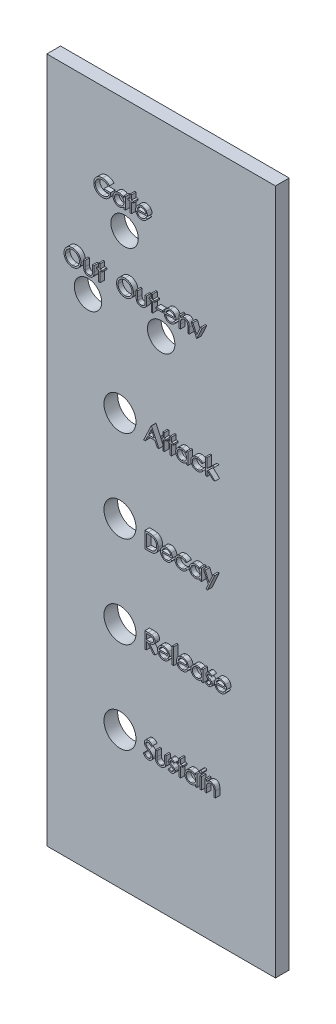
from build123d import *

# Parameters (mm, degrees)
SKETCH1_W           = 50
SKETCH1_H           = 150
SKETCH1_R           = 3
SKETCH1_R_2         = 3.5
BOSS_EXTRUDE1_DEPTH = 3
SKETCH2_W           = 1.346153846
SKETCH2_H           = 0.358974359
SKETCH2_W_2         = 0.314102564
SKETCH2_H_2         = 3.58974359
SKETCH2_H_3         = 2.557692308
BOSS_EXTRUDE2_DEPTH = 1


with BuildPart() as part:
    # Sketch1 → Boss-Extrude1 (new body)
    with BuildSketch(Plane.XY):
        Rectangle(SKETCH1_W, SKETCH1_H)
        with Locations((-16, 34)):
            Circle(SKETCH1_R, mode=Mode.SUBTRACT)
        with Locations((0, 34)):
            Circle(SKETCH1_R, mode=Mode.SUBTRACT)
        with Locations((-9, -45)):
            Circle(SKETCH1_R_2, mode=Mode.SUBTRACT)
        with Locations((-9, -25)):
            Circle(SKETCH1_R_2, mode=Mode.SUBTRACT)
        with Locations((-9, -5)):
            Circle(SKETCH1_R_2, mode=Mode.SUBTRACT)
        with Locations((-9, 15)):
            Circle(SKETCH1_R_2, mode=Mode.SUBTRACT)
        with Locations((-8, 50)):
            Circle(SKETCH1_R, mode=Mode.SUBTRACT)
    extrude(amount=BOSS_EXTRUDE1_DEPTH)

    # Sketch2 → Boss-Extrude2 (add)
    # profile 1 of 40: a face of its own
    with BuildSketch(Plane.XY.offset(3)):
        with BuildLine():
            Line((-10.275641026, 57.902644231), (-10.544871795, 57.647435897))
            add(Edge.make_bspline(
                [(-10.544871795, 57.647435897), (-10.593590683, 57.69326676), (-10.68986673, 57.783835623), (-10.846826972, 57.901346619), (-11.010590606, 58.002012719), (-11.180303103, 58.083918955), (-11.351761657, 58.149271716), (-11.522690433, 58.195799856), (-11.691336135, 58.225472393), (-11.803503353, 58.229020763), (-11.858774038, 58.230769231)],
                knots=[0, 0, 0, 0, 1.08915593, 2.152340314, 3.188132944, 4.216796309, 5.218260357, 6.173443236, 7.099959455, 8, 8, 8, 8], degree=3))
            add(Edge.make_bspline(
                [(-11.858774038, 58.230769231), (-11.892688738, 58.230355625), (-11.960430179, 58.229529486), (-12.061052123, 58.218985271), (-12.16061876, 58.203820406), (-12.258942135, 58.181878529), (-12.356213421, 58.154069469), (-12.452094313, 58.119284006), (-12.546763668, 58.078728762), (-12.639329749, 58.031866288), (-12.729070253, 57.980386442), (-12.813827088, 57.923337901), (-12.894140487, 57.862549111), (-12.968500913, 57.796498132), (-13.037336099, 57.725783266), (-13.102284471, 57.65171996), (-13.161061767, 57.572284742), (-13.214152932, 57.488939116), (-13.26151455, 57.403146926), (-13.303323204, 57.315733937), (-13.338420292, 57.226990082), (-13.366189747, 57.136804005), (-13.389100401, 57.045873415), (-13.405218008, 56.953568694), (-13.414304731, 56.859791009), (-13.415876511, 56.79699375), (-13.416666667, 56.765424679)],
                knots=[0, 0, 0, 0, 1.02818874, 2.053710826, 3.065248034, 4.081641283, 5.106893873, 6.131558223, 7.173050175, 8.228653731, 9.27666206, 10.308777013, 11.325269123, 12.329503258, 13.32196095, 14.316845687, 15.314881793, 16.315733098, 17.311955233, 18.285320748, 19.252783886, 20.203351036, 21.145449891, 22.095197417, 23.042428769, 24, 24, 24, 24], degree=3))
            add(Edge.make_bspline(
                [(-13.416666667, 56.765424679), (-13.415910948, 56.733153862), (-13.414401575, 56.668700349), (-13.404741256, 56.572506276), (-13.386813015, 56.477740874), (-13.362845307, 56.384092741), (-13.332864491, 56.291401493), (-13.295491825, 56.200068983), (-13.251226224, 56.110098592), (-13.199989672, 56.022300975), (-13.143803469, 55.936777951), (-13.080860388, 55.85621843), (-13.013999804, 55.779549652), (-12.940785905, 55.708473889), (-12.863566362, 55.641089992), (-12.780034086, 55.57925447), (-12.691831626, 55.521776247), (-12.598824414, 55.469379728), (-12.502021632, 55.422571192), (-12.402764878, 55.380947296), (-12.300737063, 55.346667959), (-12.196474373, 55.318729855), (-12.090101102, 55.295829557), (-11.981077299, 55.281097077), (-11.87020459, 55.270406246), (-11.795465958, 55.269624576), (-11.7578125, 55.269230769)],
                knots=[0, 0, 0, 0, 0.93586088, 1.869166235, 2.799637598, 3.729985548, 4.670839027, 5.622275134, 6.589130586, 7.576015415, 8.568469353, 9.55398029, 10.53834874, 11.515998671, 12.510579167, 13.508179873, 14.527009472, 15.561807829, 16.601455013, 17.643573243, 18.680854198, 19.719860599, 20.772568776, 21.833555941, 22.908541556, 24, 24, 24, 24], degree=3))
            add(Edge.make_bspline(
                [(-11.7578125, 55.269230769), (-11.712434153, 55.270179346), (-11.623326396, 55.272042029), (-11.492339953, 55.286542319), (-11.366536882, 55.309189112), (-11.246270679, 55.342355009), (-11.131401658, 55.384658684), (-11.021508717, 55.43565407), (-10.917457058, 55.49729713), (-10.818933885, 55.566870997), (-10.728176699, 55.644385829), (-10.646322575, 55.728030284), (-10.574677086, 55.817398351), (-10.512172387, 55.911963666), (-10.460463732, 56.012508971), (-10.418020937, 56.118541534), (-10.385487645, 56.230109046), (-10.372132671, 56.307200677), (-10.365384615, 56.346153846)],
                knots=[0, 0, 0, 0, 1.13008108, 2.219097802, 3.278683437, 4.311054135, 5.322181354, 6.324827112, 7.324222904, 8.330512327, 9.32562643, 10.293043162, 11.24128371, 12.174520618, 13.111833804, 14.052305215, 15.015860969, 16, 16, 16, 16], degree=3))
            Line((-10.365384615, 56.346153846), (-11.532051282, 56.346153846))
            Line((-11.532051282, 56.346153846), (-11.532051282, 56.705128205))
            Line((-11.532051282, 56.705128205), (-10.051282051, 56.705128205))
            add(Edge.make_bspline(
                [(-10.051282051, 56.705128205), (-10.0529879, 56.638220716), (-10.056326553, 56.507270675), (-10.079745469, 56.316300404), (-10.117561981, 56.13592871), (-10.169222293, 55.965965639), (-10.236097573, 55.806652046), (-10.317470102, 55.65782618), (-10.414642223, 55.520449499), (-10.524152664, 55.393400495), (-10.647052622, 55.280071283), (-10.780021242, 55.180465345), (-10.92327821, 55.09656273), (-11.076688018, 55.028302067), (-11.239748451, 54.975028073), (-11.412836831, 54.937256496), (-11.595718432, 54.914626533), (-11.721055109, 54.911735153), (-11.78515625, 54.91025641)],
                knots=[0, 0, 0, 0, 1.140356446, 2.231883559, 3.274166699, 4.278491846, 5.25512956, 6.21435461, 7.1637429, 8.11826594, 9.068280886, 10.0076534, 10.945064095, 11.891975133, 12.864533718, 13.863980011, 14.907571808, 16, 16, 16, 16], degree=3))
            add(Edge.make_bspline(
                [(-11.78515625, 54.91025641), (-11.824666385, 54.910825531), (-11.902593106, 54.911948022), (-12.017684034, 54.919925369), (-12.129601655, 54.932205946), (-12.238329664, 54.950751069), (-12.344268006, 54.973465723), (-12.446887591, 55.002552442), (-12.546579333, 55.036221141), (-12.643497319, 55.074516815), (-12.736761865, 55.118888472), (-12.826788382, 55.168198111), (-12.914074508, 55.222191472), (-12.998025673, 55.281802318), (-13.079079294, 55.346584778), (-13.156712738, 55.416668697), (-13.231360616, 55.491839816), (-13.27812108, 55.545218826), (-13.301682692, 55.572115385)],
                knots=[0, 0, 0, 0, 1.107784379, 2.184907829, 3.233506516, 4.263428166, 5.276301166, 6.270063455, 7.25232949, 8.225834625, 9.190232166, 10.146266622, 11.1027726, 12.066435141, 13.031522626, 14.010570082, 14.99756817, 16, 16, 16, 16], degree=3))
            add(Edge.make_bspline(
                [(-13.301682692, 55.572115385), (-13.335868624, 55.614786038), (-13.403673037, 55.699419055), (-13.490951193, 55.835018999), (-13.565352596, 55.975420859), (-13.625720418, 56.121015488), (-13.672858505, 56.271666701), (-13.706664758, 56.427181992), (-13.726472047, 56.587761622), (-13.729325584, 56.696426887), (-13.730769231, 56.751402244)],
                knots=[0, 0, 0, 0, 1.023165419, 2.029347347, 3.013907458, 3.994755782, 4.975994455, 5.96558838, 6.970761222, 8, 8, 8, 8], degree=3))
            add(Edge.make_bspline(
                [(-13.730769231, 56.751402244), (-13.730236993, 56.792568496), (-13.729179281, 56.874377804), (-13.716353765, 56.995835111), (-13.697952347, 57.115135803), (-13.670905292, 57.23218236), (-13.636809027, 57.347052951), (-13.594255541, 57.459800915), (-13.544710645, 57.570492787), (-13.487125149, 57.678366655), (-13.42304069, 57.781991068), (-13.353490469, 57.880948871), (-13.277486869, 57.973437936), (-13.19627107, 58.060629584), (-13.108874079, 58.141428431), (-13.016114656, 58.216582542), (-12.917921313, 58.286192728), (-12.813985133, 58.349162562), (-12.705857448, 58.405726183), (-12.593797447, 58.455315395), (-12.477839336, 58.49629871), (-12.358851858, 58.53107249), (-12.235934358, 58.55678763), (-12.109978821, 58.575436376), (-11.980328709, 58.588196975), (-11.89269268, 58.589223231), (-11.848257212, 58.58974359)],
                knots=[0, 0, 0, 0, 1.008945113, 2.00506715, 2.99143336, 3.967273523, 4.948097931, 5.927297278, 6.919902385, 7.919676788, 8.923139349, 9.905703106, 10.883022732, 11.856032218, 12.825136022, 13.798837087, 14.781400844, 15.773989409, 16.776158564, 17.77167057, 18.775803737, 19.789618931, 20.80898985, 21.851988756, 22.910860228, 24, 24, 24, 24], degree=3))
            add(Edge.make_bspline(
                [(-11.848257212, 58.58974359), (-11.812018968, 58.589164098), (-11.740162789, 58.588015034), (-11.633237057, 58.580050386), (-11.527964042, 58.567426505), (-11.424187652, 58.550199718), (-11.322261286, 58.526736028), (-11.221894581, 58.498657743), (-11.122942044, 58.46596592), (-11.025713795, 58.426977074), (-10.929556079, 58.382723449), (-10.833934239, 58.332910027), (-10.739174993, 58.276685022), (-10.645114011, 58.213881487), (-10.551158153, 58.145578069), (-10.458793511, 58.069821245), (-10.365790567, 57.989598489), (-10.305988753, 57.931916305), (-10.275641026, 57.902644231)],
                knots=[0, 0, 0, 0, 0.985871117, 1.954866573, 2.915460327, 3.869826059, 4.81536089, 5.759505086, 6.70452669, 7.649098992, 8.607881297, 9.583363685, 10.581137262, 11.603961102, 12.659522466, 13.73993555, 14.853081303, 16, 16, 16, 16], degree=3))
        make_face()
    # profile 2 of 40: a face of its own
    with BuildSketch(Plane.XY.offset(3)):
        with BuildLine():
            Line((-6.820512821, 57.557692308), (-6.820512821, 55))
            Line((-6.820512821, 55), (-7.134615385, 55))
            Line((-7.134615385, 55), (-7.134615385, 55.442407853))
            add(Edge.make_bspline(
                [(-7.134615385, 55.442407853), (-7.170034175, 55.402368259), (-7.239154391, 55.324230488), (-7.354595508, 55.222148315), (-7.476963686, 55.137769993), (-7.605665008, 55.069620078), (-7.740583251, 55.018428021), (-7.881419338, 54.982041862), (-8.028230719, 54.958648027), (-8.128483074, 54.956312005), (-8.179286859, 54.955128205)],
                knots=[0, 0, 0, 0, 1.074387032, 2.096679803, 3.090159297, 4.057316773, 5.018401886, 5.985159533, 6.978961417, 8, 8, 8, 8], degree=3))
            add(Edge.make_bspline(
                [(-8.179286859, 54.955128205), (-8.224454813, 54.956354577), (-8.313528018, 54.958773038), (-8.444557095, 54.977535341), (-8.570649344, 55.007665963), (-8.691923917, 55.049566853), (-8.807596062, 55.105147674), (-8.918656159, 55.171688922), (-9.024528851, 55.250929752), (-9.12360039, 55.341517781), (-9.21483239, 55.439912768), (-9.294893663, 55.544858315), (-9.361646743, 55.655900619), (-9.417466824, 55.771633773), (-9.460463168, 55.892948692), (-9.490436802, 56.01942586), (-9.509177249, 56.150915734), (-9.51159471, 56.240455257), (-9.512820513, 56.285857372)],
                knots=[0, 0, 0, 0, 1.033919861, 2.038935746, 3.024066025, 3.998881131, 4.97069526, 5.957263378, 6.95902576, 7.993208707, 9.027059324, 10.027763471, 11.009749337, 11.988697705, 12.965288445, 13.950418724, 14.960734635, 16, 16, 16, 16], degree=3))
            add(Edge.make_bspline(
                [(-9.512820513, 56.285857372), (-9.511567541, 56.330321075), (-9.509090485, 56.418223419), (-9.490637265, 56.547502117), (-9.459606256, 56.672020377), (-9.416058408, 56.791377321), (-9.360216453, 56.905717371), (-9.292288366, 57.015121396), (-9.212269242, 57.119890793), (-9.120016835, 57.21756202), (-9.020082065, 57.307782634), (-8.913173334, 57.38619168), (-8.801950052, 57.453908529), (-8.684687042, 57.507562005), (-8.563119937, 57.550971109), (-8.436166491, 57.581004078), (-8.304354913, 57.598701399), (-8.214864421, 57.601264163), (-8.169471154, 57.602564103)],
                knots=[0, 0, 0, 0, 1.020392517, 2.01726096, 2.990465484, 3.961182959, 4.928053699, 5.906110375, 6.912531644, 7.948652711, 8.985773172, 9.998621852, 10.987621588, 11.969261332, 12.953316658, 13.946091881, 14.958173133, 16, 16, 16, 16], degree=3))
            add(Edge.make_bspline(
                [(-8.169471154, 57.602564103), (-8.117271295, 57.601126351), (-8.014909835, 57.598306988), (-7.865181826, 57.574844261), (-7.723537348, 57.535205794), (-7.588882996, 57.481288296), (-7.46170231, 57.409639567), (-7.343199325, 57.319259606), (-7.232133842, 57.210718419), (-7.16775355, 57.127347974), (-7.134615385, 57.084435096)],
                knots=[0, 0, 0, 0, 1.038897134, 2.037228247, 3.008116434, 3.962042015, 4.918381754, 5.904844433, 6.921570401, 8, 8, 8, 8], degree=3))
            Line((-7.134615385, 57.084435096), (-7.134615385, 57.557692308))
            Line((-7.134615385, 57.557692308), (-6.820512821, 57.557692308))
        make_face()
        with BuildLine():
            add(Edge.make_bspline(
                [(-8.165264423, 57.288461538), (-8.211178761, 57.286827901), (-8.301806361, 57.28360336), (-8.434850363, 57.258429865), (-8.562163777, 57.21654527), (-8.683109851, 57.159263369), (-8.795778068, 57.087234632), (-8.896471739, 57.000113249), (-8.98601444, 56.900276235), (-9.061322704, 56.788174125), (-9.122713201, 56.667996033), (-9.165880233, 56.542371595), (-9.194349481, 56.413566618), (-9.197258001, 56.326203932), (-9.198717949, 56.282351763)],
                knots=[0, 0, 0, 0, 1.031046209, 2.035121221, 3.029706178, 4.034933723, 5.034054252, 6.02443088, 7.017295772, 8.038157696, 9.050218397, 10.03989886, 11.016116709, 12, 12, 12, 12], degree=3))
            add(Edge.make_bspline(
                [(-9.198717949, 56.282351763), (-9.196853055, 56.238761656), (-9.193130579, 56.1517523), (-9.166379884, 56.022771723), (-9.121500011, 55.897117681), (-9.060257948, 55.775856687), (-8.983571323, 55.663272587), (-8.894682671, 55.561532464), (-8.792732389, 55.474042876), (-8.679804882, 55.400805303), (-8.559196912, 55.341642782), (-8.43236298, 55.300477142), (-8.301687342, 55.273899362), (-8.212835008, 55.270794885), (-8.16806891, 55.269230769)],
                knots=[0, 0, 0, 0, 0.979072187, 1.954306742, 2.945804271, 3.96968567, 4.997920485, 5.998718438, 6.996577872, 8.005894225, 9.015743152, 10.005417472, 10.995077863, 12, 12, 12, 12], degree=3))
            add(Edge.make_bspline(
                [(-8.16806891, 55.269230769), (-8.122622407, 55.270890733), (-8.032233821, 55.274192237), (-7.898795113, 55.299473502), (-7.76930015, 55.3412423), (-7.645512922, 55.399141427), (-7.530196791, 55.470898783), (-7.426698913, 55.554905874), (-7.339182945, 55.652609058), (-7.264990335, 55.759985511), (-7.206814919, 55.877697508), (-7.164438859, 56.003031698), (-7.139384954, 56.135992447), (-7.136227224, 56.226856374), (-7.134615385, 56.273237179)],
                knots=[0, 0, 0, 0, 1.01762866, 2.023962475, 3.030623092, 4.058876274, 5.077231937, 6.066672613, 7.034107872, 8.005628644, 8.981990164, 9.965428785, 10.961468474, 12, 12, 12, 12], degree=3))
            add(Edge.make_bspline(
                [(-7.134615385, 56.273237179), (-7.135575041, 56.30857501), (-7.137463948, 56.378131043), (-7.151894518, 56.480258561), (-7.174849444, 56.577992287), (-7.207195614, 56.671434976), (-7.249686899, 56.760069991), (-7.300934665, 56.844533752), (-7.361840114, 56.924386963), (-7.431422811, 56.998530034), (-7.507588013, 57.066156496), (-7.588182554, 57.126520737), (-7.674161301, 57.17610951), (-7.764078338, 57.217150781), (-7.858089672, 57.249809931), (-7.956960292, 57.271597625), (-8.059639279, 57.286557946), (-8.129685334, 57.287820327), (-8.165264423, 57.288461538)],
                knots=[0, 0, 0, 0, 1.050140795, 2.067009409, 3.05949893, 4.030605086, 5.00011959, 5.97591094, 6.962425594, 7.979863591, 8.993523472, 9.986985069, 10.967611495, 11.937549037, 12.921786183, 13.919465291, 14.943216303, 16, 16, 16, 16], degree=3))
        make_face(mode=Mode.SUBTRACT)
    # profile 3 of 40: a face of its own
    with BuildSketch(Plane.XY.offset(3)):
        Polygon((-5.788461538, 58.58974359), (-5.474358974, 58.58974359), (-5.474358974, 57.557692308), (-5.025641026, 57.557692308), (-5.025641026, 57.243589744), (-5.474358974, 57.243589744), (-5.474358974, 55), (-5.788461538, 55), (-5.788461538, 57.243589744), (-6.237179487, 57.243589744), (-6.237179487, 57.557692308), (-5.788461538, 57.557692308), align=None)
    # profile 4 of 40: a face of its own
    with BuildSketch(Plane.XY.offset(3)):
        with BuildLine():
            Line((-2.388020833, 55.807692308), (-2.108974359, 55.661157853))
            add(Edge.make_bspline(
                [(-2.108974359, 55.661157853), (-2.131210954, 55.621714521), (-2.174474563, 55.544973418), (-2.248875311, 55.439541558), (-2.326867383, 55.344693842), (-2.411971351, 55.262964188), (-2.50164103, 55.191712803), (-2.596373685, 55.129374978), (-2.696662503, 55.076256458), (-2.802512227, 55.03150393), (-2.914811779, 54.997094436), (-3.033833295, 54.972790215), (-3.15980479, 54.957766946), (-3.24615097, 54.956021806), (-3.290364583, 54.955128205)],
                knots=[0, 0, 0, 0, 1.120438281, 2.179929193, 3.190490725, 4.156257408, 5.095198341, 6.022838206, 6.959905092, 7.901321166, 8.864066838, 9.862729781, 10.905609505, 12, 12, 12, 12], degree=3))
            add(Edge.make_bspline(
                [(-3.290364583, 54.955128205), (-3.339506561, 54.95627538), (-3.435368323, 54.958513187), (-3.57490807, 54.977805652), (-3.706287488, 55.00927801), (-3.829499191, 55.053243552), (-3.944241444, 55.110670876), (-4.050742299, 55.180630358), (-4.149561825, 55.262762612), (-4.237586034, 55.357779056), (-4.316829917, 55.459461013), (-4.386755737, 55.565416898), (-4.445213168, 55.675380122), (-4.492765778, 55.788650646), (-4.531170643, 55.90451454), (-4.557937347, 56.024026007), (-4.573367094, 56.146861592), (-4.57573154, 56.229958927), (-4.576923077, 56.271834936)],
                knots=[0, 0, 0, 0, 1.145258523, 2.234067595, 3.276747158, 4.290159414, 5.277019952, 6.260822364, 7.254936242, 8.264827045, 9.274100331, 10.257902744, 11.220704747, 12.172965371, 13.118907548, 14.062713208, 15.023725156, 16, 16, 16, 16], degree=3))
            add(Edge.make_bspline(
                [(-4.576923077, 56.271834936), (-4.575863936, 56.311129766), (-4.573764857, 56.389006931), (-4.56053407, 56.504272476), (-4.537085777, 56.616300928), (-4.504909453, 56.725185376), (-4.463358207, 56.83074351), (-4.412525988, 56.933039574), (-4.35233361, 57.031964713), (-4.305860936, 57.094367847), (-4.282451923, 57.125801282)],
                knots=[0, 0, 0, 0, 1.024358464, 2.0301432, 3.019427413, 4.004406732, 4.986367066, 5.972626655, 6.978780325, 8, 8, 8, 8], degree=3))
            add(Edge.make_bspline(
                [(-4.282451923, 57.125801282), (-4.25074424, 57.163670152), (-4.188333294, 57.238208303), (-4.082776938, 57.336146628), (-3.968476742, 57.418190404), (-3.846865116, 57.48619754), (-3.716528642, 57.537871187), (-3.579219351, 57.576378769), (-3.433373765, 57.59795678), (-3.333668544, 57.601004614), (-3.282652244, 57.602564103)],
                knots=[0, 0, 0, 0, 1.030682036, 2.02871468, 2.997146059, 3.962720338, 4.930598197, 5.918074684, 6.934738563, 8, 8, 8, 8], degree=3))
            add(Edge.make_bspline(
                [(-3.282652244, 57.602564103), (-3.230204638, 57.601210054), (-3.127314392, 57.598553718), (-2.977282271, 57.573927385), (-2.835321555, 57.53487483), (-2.70148905, 57.47972104), (-2.57577119, 57.408561488), (-2.45898514, 57.320419647), (-2.349133628, 57.218001559), (-2.285225049, 57.13923835), (-2.252704327, 57.099158654)],
                knots=[0, 0, 0, 0, 1.056321875, 2.072262726, 3.055038591, 4.01806755, 4.982017516, 5.957941055, 6.960871419, 8, 8, 8, 8], degree=3))
            add(Edge.make_bspline(
                [(-2.252704327, 57.099158654), (-2.230577389, 57.068955072), (-2.186470796, 57.008748954), (-2.131223695, 56.910577797), (-2.0832663, 56.807867202), (-2.044933339, 56.698956905), (-2.013893838, 56.585137325), (-1.99143702, 56.46559478), (-1.978267401, 56.340364869), (-1.975678704, 56.255038314), (-1.974358974, 56.211538462)],
                knots=[0, 0, 0, 0, 0.94817472, 1.890038105, 2.849395472, 3.817997239, 4.812318967, 5.836947057, 6.897266129, 8, 8, 8, 8], degree=3))
            Line((-1.974358974, 56.211538462), (-4.262820513, 56.211538462))
            add(Edge.make_bspline(
                [(-4.262820513, 56.211538462), (-4.261280906, 56.177837997), (-4.258253332, 56.111567394), (-4.244138189, 56.01459661), (-4.221889416, 55.922223268), (-4.190620353, 55.835140226), (-4.152753508, 55.752210099), (-4.106367791, 55.674048062), (-4.051028237, 55.601010132), (-3.989302537, 55.532442994), (-3.920595442, 55.471382233), (-3.848312695, 55.416730457), (-3.77141913, 55.37092486), (-3.690521046, 55.33374497), (-3.605749261, 55.304638654), (-3.517077066, 55.284770834), (-3.42467895, 55.271463727), (-3.361693216, 55.269984061), (-3.329627404, 55.269230769)],
                knots=[0, 0, 0, 0, 1.094153842, 2.151609401, 3.174256925, 4.172055639, 5.149267565, 6.128595816, 7.11444997, 8.118368179, 9.117203808, 10.09244225, 11.054858984, 12.015122123, 12.976791628, 13.957293641, 14.960065497, 16, 16, 16, 16], degree=3))
            add(Edge.make_bspline(
                [(-3.329627404, 55.269230769), (-3.298276256, 55.269838826), (-3.236069565, 55.271045327), (-3.143428708, 55.282777238), (-3.052289181, 55.301747513), (-2.963028197, 55.327637504), (-2.877457351, 55.359214356), (-2.798211801, 55.397317213), (-2.725331586, 55.43946696), (-2.657214619, 55.487676635), (-2.591143626, 55.546684822), (-2.525601139, 55.620320543), (-2.455324486, 55.707408071), (-2.411334893, 55.772953737), (-2.388020833, 55.807692308)],
                knots=[0, 0, 0, 0, 0.99110716, 1.966546729, 2.947904876, 3.932708344, 4.903319531, 5.828989031, 6.710028674, 7.56322171, 8.463672341, 9.504779593, 10.677557249, 12, 12, 12, 12], degree=3))
        make_face()
        with BuildLine():
            add(Edge.make_bspline(
                [(-2.288461538, 56.525641026), (-2.299958163, 56.567303899), (-2.322085464, 56.64749152), (-2.368321829, 56.75853241), (-2.42039337, 56.857220311), (-2.482015101, 56.942799944), (-2.551833827, 57.018803457), (-2.632479009, 57.085222043), (-2.722914903, 57.144639494), (-2.822674043, 57.194791993), (-2.928315829, 57.237481852), (-3.038922021, 57.266106968), (-3.151779808, 57.28571651), (-3.228114095, 57.287542618), (-3.266526442, 57.288461538)],
                knots=[0, 0, 0, 0, 1.154881502, 2.222775134, 3.210006277, 4.132804581, 5.035138423, 5.962687519, 6.919655026, 7.923214229, 8.944639381, 9.960483929, 10.97369054, 12, 12, 12, 12], degree=3))
            add(Edge.make_bspline(
                [(-3.266526442, 57.288461538), (-3.297875881, 57.287849867), (-3.35984713, 57.286640721), (-3.451148198, 57.275170592), (-3.538827897, 57.256210747), (-3.623533185, 57.23024579), (-3.704154053, 57.195637188), (-3.782348821, 57.155053961), (-3.856129217, 57.105512377), (-3.902270513, 57.067753522), (-3.925580929, 57.048677885)],
                knots=[0, 0, 0, 0, 1.04873581, 2.073130211, 3.073294108, 4.04793562, 5.032784715, 6.005352987, 6.992311501, 8, 8, 8, 8], degree=3))
            add(Edge.make_bspline(
                [(-3.925580929, 57.048677885), (-3.942274211, 57.033583569), (-3.976057346, 57.003036353), (-4.021197867, 56.950407146), (-4.06441834, 56.893655584), (-4.103751993, 56.83061046), (-4.139829579, 56.761989681), (-4.173589556, 56.688372045), (-4.203975968, 56.609198915), (-4.221072078, 56.554026476), (-4.229867788, 56.525641026)],
                knots=[0, 0, 0, 0, 0.879870761, 1.780643979, 2.707998968, 3.669668524, 4.684282772, 5.740141944, 6.837334558, 8, 8, 8, 8], degree=3))
            Line((-4.229867788, 56.525641026), (-2.288461538, 56.525641026))
        make_face(mode=Mode.SUBTRACT)
    # profile 5 of 40: a face of its own
    with BuildSketch(Plane.XY.offset(3)):
        with BuildLine():
            add(Edge.make_bspline(
                [(-18.413461538, 42.08974359), (-18.348653433, 42.08810211), (-18.221364966, 42.084878109), (-18.034290068, 42.060199006), (-17.855694973, 42.017503616), (-17.684124834, 41.960640633), (-17.521631857, 41.884786248), (-17.366992965, 41.7931011), (-17.220576091, 41.684624641), (-17.084354709, 41.560195414), (-16.959697759, 41.42481196), (-16.849871873, 41.28033405), (-16.757829579, 41.127635248), (-16.682243792, 40.967174417), (-16.622945182, 40.799314449), (-16.582026139, 40.623160446), (-16.555887988, 40.439853756), (-16.552832211, 40.314826892), (-16.551282051, 40.251402244)],
                knots=[0, 0, 0, 0, 1.065120563, 2.091984664, 3.0946048, 4.079830382, 5.057816894, 6.036188127, 7.030412546, 8.04752943, 9.064399622, 10.05169764, 11.02544977, 11.989514704, 12.962713494, 13.945757189, 14.957906945, 16, 16, 16, 16], degree=3))
            add(Edge.make_bspline(
                [(-16.551282051, 40.251402244), (-16.552831984, 40.188444797), (-16.55588708, 40.064348377), (-16.582055858, 39.882204933), (-16.623096858, 39.707114236), (-16.681693124, 39.539368583), (-16.756918603, 39.37879102), (-16.849573774, 39.225804066), (-16.958714984, 39.080357567), (-17.082921835, 38.944044902), (-17.218322877, 38.819047431), (-17.363553144, 38.710128556), (-17.515346464, 38.616404431), (-17.675656172, 38.541620757), (-17.842356209, 38.481848837), (-18.016938532, 38.441096207), (-18.198585086, 38.414809163), (-18.32245609, 38.411790647), (-18.385416667, 38.41025641)],
                knots=[0, 0, 0, 0, 1.043624062, 2.057103931, 3.04512605, 4.022047818, 4.998200453, 5.980619268, 6.982898556, 8.009068085, 9.034988726, 10.034168286, 11.015286542, 11.987931943, 12.962482838, 13.94673481, 14.956375938, 16, 16, 16, 16], degree=3))
            add(Edge.make_bspline(
                [(-18.385416667, 38.41025641), (-18.448840986, 38.411805797), (-18.573867202, 38.414860051), (-18.757404237, 38.441041456), (-18.933681981, 38.48198276), (-19.102196332, 38.540492196), (-19.263041262, 38.616109427), (-19.416531344, 38.708313806), (-19.562050492, 38.817720947), (-19.698392238, 38.941887521), (-19.823141436, 39.077059073), (-19.931900812, 39.221893329), (-20.024125925, 39.373548785), (-20.099489258, 39.532446309), (-20.159153717, 39.697817752), (-20.199858535, 39.870766229), (-20.226194487, 40.050305735), (-20.229229334, 40.172548634), (-20.230769231, 40.234575321)],
                knots=[0, 0, 0, 0, 1.053102029, 2.075944431, 3.073151272, 4.055350789, 5.033113405, 6.020478099, 7.024410459, 8.052272461, 9.079885166, 10.07527673, 11.055994387, 12.023226415, 12.992069828, 13.970394897, 14.97016774, 16, 16, 16, 16], degree=3))
            add(Edge.make_bspline(
                [(-20.230769231, 40.234575321), (-20.230234595, 40.27620799), (-20.229172069, 40.358948113), (-20.216380376, 40.481814713), (-20.197818675, 40.602705371), (-20.171216763, 40.721276319), (-20.136425096, 40.837237304), (-20.095373068, 40.951388067), (-20.045233223, 41.06257179), (-19.988552575, 41.171315182), (-19.925290767, 41.275923088), (-19.855415017, 41.374802671), (-19.781379649, 41.468783668), (-19.700216255, 41.555430672), (-19.61459981, 41.637264328), (-19.523141432, 41.713027045), (-19.426399188, 41.783401996), (-19.323956808, 41.846822337), (-19.218338533, 41.904181472), (-19.109461755, 41.953403323), (-18.998805184, 41.995649384), (-18.885850536, 42.029890209), (-18.770897764, 42.056922245), (-18.653695979, 42.075329599), (-18.534338553, 42.088153917), (-18.453927234, 42.089211419), (-18.413461538, 42.08974359)],
                knots=[0, 0, 0, 0, 1.037015668, 2.060948919, 3.074880161, 4.083647147, 5.086022904, 6.090072063, 7.104153813, 8.122640571, 9.144368836, 10.147691507, 11.138137339, 12.123020368, 13.103399296, 14.087645067, 15.080126199, 16.082011238, 17.087798457, 18.072939717, 19.057185487, 20.037253025, 21.01195951, 21.997135196, 22.992090687, 24, 24, 24, 24], degree=3))
        make_face()
        with BuildLine():
            add(Edge.make_bspline(
                [(-18.398036859, 41.730769231), (-18.431251493, 41.730364341), (-18.497363225, 41.729558431), (-18.595647762, 41.718942715), (-18.692639696, 41.703812826), (-18.788359058, 41.682231305), (-18.882405347, 41.652827253), (-18.975655188, 41.618986345), (-19.067258242, 41.577765254), (-19.1569121, 41.53119255), (-19.243827175, 41.479643629), (-19.325839877, 41.422671862), (-19.403162521, 41.361613307), (-19.475605787, 41.29632547), (-19.542956959, 41.226475868), (-19.606541661, 41.153123432), (-19.663811242, 41.074171541), (-19.716296819, 40.991761134), (-19.76326466, 40.905999553), (-19.805030014, 40.817789691), (-19.839194023, 40.726412004), (-19.867056399, 40.632857846), (-19.89015621, 40.537275387), (-19.904790134, 40.438939538), (-19.915522494, 40.338344426), (-19.916282339, 40.270362572), (-19.916666667, 40.235977564)],
                knots=[0, 0, 0, 0, 1.008559885, 2.007477868, 2.99961109, 3.989939068, 4.984837346, 5.991145699, 7.001802488, 8.033829008, 9.059044045, 10.069351652, 11.065060232, 12.050310815, 13.029377138, 14.011219647, 14.996725999, 15.989392538, 16.977580475, 17.965360261, 18.951710183, 19.937753436, 20.929683414, 21.935841486, 22.955955122, 24, 24, 24, 24], degree=3))
            add(Edge.make_bspline(
                [(-19.916666667, 40.235977564), (-19.915391805, 40.185415343), (-19.912883757, 40.085943813), (-19.890926187, 39.940175669), (-19.857104212, 39.800087383), (-19.807246846, 39.666445474), (-19.744896231, 39.538101191), (-19.667869341, 39.416193086), (-19.576610255, 39.300688212), (-19.472946729, 39.192392943), (-19.359624022, 39.093547138), (-19.239291292, 39.00678373), (-19.113237685, 38.93337348), (-18.981134482, 38.873568408), (-18.843686943, 38.82617867), (-18.700009392, 38.793700039), (-18.551058932, 38.772324583), (-18.449528277, 38.770271827), (-18.398036859, 38.769230769)],
                knots=[0, 0, 0, 0, 1.032063989, 2.030389145, 3.003944642, 3.970395727, 4.937377036, 5.913328081, 6.909231446, 7.93887556, 8.970685674, 9.976071282, 10.964166581, 11.944589148, 12.933237628, 13.927779006, 14.949070134, 16, 16, 16, 16], degree=3))
            add(Edge.make_bspline(
                [(-18.398036859, 38.769230769), (-18.363427357, 38.769706274), (-18.294786321, 38.770649342), (-18.192690799, 38.780148018), (-18.092434587, 38.795379888), (-17.994158307, 38.817310543), (-17.897973496, 38.84475775), (-17.803478693, 38.877365478), (-17.711680402, 38.918046682), (-17.621420564, 38.962994633), (-17.535024323, 39.014234791), (-17.45254879, 39.06927294), (-17.376072811, 39.130241561), (-17.303683739, 39.194559374), (-17.23605605, 39.263523221), (-17.173647066, 39.337043443), (-17.116666934, 39.4155841), (-17.064201287, 39.497869506), (-17.017398024, 39.583865759), (-16.976618925, 39.672395437), (-16.94202281, 39.763240546), (-16.914094305, 39.856532118), (-16.892208843, 39.952092966), (-16.877128923, 40.050051045), (-16.866580484, 40.150210387), (-16.865785407, 40.217954243), (-16.865384615, 40.252103365)],
                knots=[0, 0, 0, 0, 1.047197238, 2.076906641, 3.100256066, 4.114471768, 5.12198147, 6.126382909, 7.136867548, 8.15857795, 9.17633901, 10.174870724, 11.156907918, 12.133735059, 13.104061851, 14.077631395, 15.04955518, 16.038496417, 17.029181396, 18.010275684, 18.986308667, 19.968651475, 20.955262928, 21.950658345, 22.966943676, 24, 24, 24, 24], degree=3))
            add(Edge.make_bspline(
                [(-16.865384615, 40.252103365), (-16.865785728, 40.28601887), (-16.86658141, 40.35329652), (-16.877123884, 40.452757338), (-16.892224775, 40.55001055), (-16.913987483, 40.644674353), (-16.942037637, 40.736772878), (-16.976624967, 40.826219625), (-17.017410266, 40.913347821), (-17.064218491, 40.997942118), (-17.116834314, 41.079116855), (-17.174328558, 41.156719268), (-17.237693906, 41.229292009), (-17.305119931, 41.298626703), (-17.378290816, 41.363244593), (-17.45687511, 41.423167114), (-17.539918788, 41.479840388), (-17.627846023, 41.53096595), (-17.718589977, 41.578180182), (-17.811703935, 41.618631186), (-17.906133035, 41.653003305), (-18.001637147, 41.68232027), (-18.099020125, 41.7037283), (-18.197623954, 41.71895635), (-18.297312213, 41.729554736), (-18.364355432, 41.730363114), (-18.398036859, 41.730769231)],
                knots=[0, 0, 0, 0, 1.02996197, 2.043119294, 3.035359645, 4.018872909, 4.991431989, 5.957985074, 6.929999688, 7.912076566, 8.892894881, 9.867085534, 10.843653904, 11.817741046, 12.803660682, 13.806313499, 14.818574707, 15.856120519, 16.894564902, 17.924820532, 18.937903209, 19.946497019, 20.957711757, 21.963978472, 22.977135795, 24, 24, 24, 24], degree=3))
        make_face(mode=Mode.SUBTRACT)
    # profile 6 of 40: a face of its own
    with BuildSketch(Plane.XY.offset(3)):
        with BuildLine():
            Line((-15.967948718, 41.057692308), (-15.653846154, 41.057692308))
            Line((-15.653846154, 41.057692308), (-15.653846154, 39.871394231))
            add(Edge.make_bspline(
                [(-15.653846154, 39.871394231), (-15.653704249, 39.836571482), (-15.653432792, 39.769957194), (-15.651591851, 39.674102007), (-15.647261757, 39.586685294), (-15.641847932, 39.507656557), (-15.634885796, 39.437029166), (-15.626602436, 39.375049809), (-15.617344014, 39.321015625), (-15.6082813, 39.288472269), (-15.604066506, 39.27333734)],
                knots=[0, 0, 0, 0, 1.388932606, 2.656963016, 3.823490214, 4.879454478, 5.816252168, 6.653371382, 7.373723809, 8, 8, 8, 8], degree=3))
            add(Edge.make_bspline(
                [(-15.604066506, 39.27333734), (-15.597305051, 39.254314469), (-15.58392271, 39.216664208), (-15.559649227, 39.162275202), (-15.52962089, 39.11189992), (-15.496761062, 39.063595847), (-15.458861655, 39.01879386), (-15.416402183, 38.977569617), (-15.370803946, 38.938365526), (-15.303048923, 38.891980734), (-15.210389657, 38.842265403), (-15.088736902, 38.799369585), (-14.956832676, 38.773733765), (-14.865667957, 38.77075951), (-14.818810096, 38.769230769)],
                knots=[0, 0, 0, 0, 0.725840625, 1.436591201, 2.137033971, 2.831655856, 3.53531722, 4.242432219, 4.957935707, 5.694543706, 7.190802206, 8.724350549, 10.316345118, 12, 12, 12, 12], degree=3))
            add(Edge.make_bspline(
                [(-14.818810096, 38.769230769), (-14.771956588, 38.770792018), (-14.68130372, 38.773812745), (-14.550848751, 38.798596284), (-14.431597336, 38.840001973), (-14.324746385, 38.897809384), (-14.230780545, 38.968551447), (-14.152476126, 39.051560256), (-14.087868872, 39.144209643), (-14.059659451, 39.213333922), (-14.045472756, 39.248096955)],
                knots=[0, 0, 0, 0, 1.157059328, 2.238695713, 3.266970494, 4.264342957, 5.228770407, 6.160125903, 7.074715775, 8, 8, 8, 8], degree=3))
            add(Edge.make_bspline(
                [(-14.045472756, 39.248096955), (-14.041278526, 39.262063254), (-14.032006108, 39.292939329), (-14.022043756, 39.345319078), (-14.013069295, 39.407783682), (-14.005406119, 39.480741891), (-13.999940956, 39.564003043), (-13.99699493, 39.657541119), (-13.993666654, 39.76106248), (-13.993616138, 39.833530239), (-13.993589744, 39.871394231)],
                knots=[0, 0, 0, 0, 0.557542046, 1.232589297, 2.036731608, 2.971723315, 4.038036528, 5.22795436, 6.551621927, 8, 8, 8, 8], degree=3))
            Line((-13.993589744, 39.871394231), (-13.993589744, 41.057692308))
            Line((-13.993589744, 41.057692308), (-13.679487179, 41.057692308))
            Line((-13.679487179, 41.057692308), (-13.679487179, 39.8125))
            add(Edge.make_bspline(
                [(-13.679487179, 39.8125), (-13.679928874, 39.770192829), (-13.680785823, 39.688111129), (-13.686293166, 39.568827017), (-13.695742779, 39.457664772), (-13.710085464, 39.354565552), (-13.726951138, 39.259608071), (-13.748707411, 39.172670625), (-13.774685649, 39.094021071), (-13.803991164, 39.022279294), (-13.838613032, 38.9572324), (-13.875440052, 38.895496583), (-13.917964824, 38.838603648), (-13.962735058, 38.783721511), (-14.012536714, 38.733579983), (-14.066436573, 38.687028507), (-14.123675993, 38.643355476), (-14.185525191, 38.604264196), (-14.251081254, 38.569047551), (-14.320425111, 38.537831473), (-14.394406109, 38.513128896), (-14.472069746, 38.49181823), (-14.553796525, 38.475103761), (-14.639507658, 38.463317194), (-14.729174275, 38.456091863), (-14.790283734, 38.455454818), (-14.821614583, 38.455128205)],
                knots=[0, 0, 0, 0, 1.493040784, 2.896703357, 4.213163133, 5.428574705, 6.569057535, 7.615249723, 8.588095153, 9.490268104, 10.346124644, 11.18633936, 12.024365274, 12.850166724, 13.684164916, 14.514361689, 15.362232829, 16.222528818, 17.093394965, 17.986930858, 18.902426812, 19.842810585, 20.827885679, 21.843828298, 22.894529745, 24, 24, 24, 24], degree=3))
            add(Edge.make_bspline(
                [(-14.821614583, 38.455128205), (-14.852711097, 38.455467912), (-14.913818643, 38.456135468), (-15.003489887, 38.463277276), (-15.089438493, 38.475085447), (-15.171358892, 38.491940664), (-15.249333289, 38.512979734), (-15.323677529, 38.53798327), (-15.393521092, 38.569063751), (-15.459703096, 38.604041309), (-15.521705484, 38.643606584), (-15.579814062, 38.686974624), (-15.633950915, 38.734080687), (-15.684127983, 38.784728044), (-15.729640959, 38.83954498), (-15.771057001, 38.898090541), (-15.809013706, 38.959784629), (-15.843366496, 39.025847792), (-15.872878252, 39.098419802), (-15.898933498, 39.178716899), (-15.920244136, 39.267619415), (-15.937586605, 39.365051344), (-15.951538045, 39.470546385), (-15.961224187, 39.584714801), (-15.966640018, 39.707278493), (-15.96750308, 39.791928383), (-15.967948718, 39.835637019)],
                knots=[0, 0, 0, 0, 1.083640291, 2.129454052, 3.13281866, 4.105697902, 5.042300162, 5.946461698, 6.836384745, 7.703652036, 8.553297018, 9.397182691, 10.228592656, 11.052265423, 11.879314572, 12.708807002, 13.549817954, 14.402308542, 15.300838682, 16.27712199, 17.341985831, 18.484375296, 19.725102775, 21.0496083, 22.476576903, 24, 24, 24, 24], degree=3))
            Line((-15.967948718, 39.835637019), (-15.967948718, 41.057692308))
        make_face()
    # profile 7 of 40: a face of its own
    with BuildSketch(Plane.XY.offset(3)):
        Polygon((-12.647435897, 42.08974359), (-12.333333333, 42.08974359), (-12.333333333, 41.057692308), (-11.884615385, 41.057692308), (-11.884615385, 40.743589744), (-12.333333333, 40.743589744), (-12.333333333, 38.5), (-12.647435897, 38.5), (-12.647435897, 40.743589744), (-13.096153846, 40.743589744), (-13.096153846, 41.057692308), (-12.647435897, 41.057692308), align=None)
    # profile 8 of 40: a face of its own
    with BuildSketch(Plane.XY.offset(3)):
        with BuildLine():
            add(Edge.make_bspline(
                [(-6.926282051, 42.08974359), (-6.861473945, 42.08810211), (-6.734185478, 42.084878109), (-6.547110581, 42.060199006), (-6.368515485, 42.017503616), (-6.196945347, 41.960640633), (-6.03445237, 41.884786248), (-5.879813478, 41.7931011), (-5.733396604, 41.684624641), (-5.597175222, 41.560195414), (-5.472518272, 41.42481196), (-5.362692386, 41.28033405), (-5.270650092, 41.127635248), (-5.195064305, 40.967174417), (-5.135765695, 40.799314449), (-5.094846651, 40.623160446), (-5.068708501, 40.439853756), (-5.065652724, 40.314826892), (-5.064102564, 40.251402244)],
                knots=[0, 0, 0, 0, 1.065120563, 2.091984664, 3.0946048, 4.079830382, 5.057816894, 6.036188127, 7.030412546, 8.04752943, 9.064399622, 10.05169764, 11.02544977, 11.989514704, 12.962713494, 13.945757189, 14.957906945, 16, 16, 16, 16], degree=3))
            add(Edge.make_bspline(
                [(-5.064102564, 40.251402244), (-5.065652497, 40.188444797), (-5.068707593, 40.064348377), (-5.094876371, 39.882204933), (-5.135917371, 39.707114236), (-5.194513637, 39.539368583), (-5.269739115, 39.37879102), (-5.362394286, 39.225804066), (-5.471535497, 39.080357567), (-5.595742348, 38.944044902), (-5.73114339, 38.819047431), (-5.876373657, 38.710128556), (-6.028166977, 38.616404431), (-6.188476685, 38.541620757), (-6.355176722, 38.481848837), (-6.529759045, 38.441096207), (-6.711405599, 38.414809163), (-6.835276603, 38.411790647), (-6.898237179, 38.41025641)],
                knots=[0, 0, 0, 0, 1.043624062, 2.057103931, 3.04512605, 4.022047818, 4.998200453, 5.980619268, 6.982898556, 8.009068085, 9.034988726, 10.034168286, 11.015286542, 11.987931943, 12.962482838, 13.94673481, 14.956375938, 16, 16, 16, 16], degree=3))
            add(Edge.make_bspline(
                [(-6.898237179, 38.41025641), (-6.961661498, 38.411805797), (-7.086687714, 38.414860051), (-7.27022475, 38.441041456), (-7.446502494, 38.48198276), (-7.615016845, 38.540492196), (-7.775861774, 38.616109427), (-7.929351857, 38.708313806), (-8.074871004, 38.817720947), (-8.211212751, 38.941887521), (-8.335961949, 39.077059073), (-8.444721325, 39.221893329), (-8.536946438, 39.373548785), (-8.612309771, 39.532446309), (-8.67197423, 39.697817752), (-8.712679048, 39.870766229), (-8.739015, 40.050305735), (-8.742049847, 40.172548634), (-8.743589744, 40.234575321)],
                knots=[0, 0, 0, 0, 1.053102029, 2.075944431, 3.073151272, 4.055350789, 5.033113405, 6.020478099, 7.024410459, 8.052272461, 9.079885166, 10.07527673, 11.055994387, 12.023226415, 12.992069828, 13.970394897, 14.97016774, 16, 16, 16, 16], degree=3))
            add(Edge.make_bspline(
                [(-8.743589744, 40.234575321), (-8.743055108, 40.27620799), (-8.741992582, 40.358948113), (-8.729200889, 40.481814713), (-8.710639188, 40.602705371), (-8.684037276, 40.721276319), (-8.649245609, 40.837237304), (-8.608193581, 40.951388067), (-8.558053736, 41.06257179), (-8.501373088, 41.171315182), (-8.43811128, 41.275923088), (-8.36823553, 41.374802671), (-8.294200162, 41.468783668), (-8.213036768, 41.555430672), (-8.127420323, 41.637264328), (-8.035961945, 41.713027045), (-7.9392197, 41.783401996), (-7.836777321, 41.846822337), (-7.731159046, 41.904181472), (-7.622282268, 41.953403323), (-7.511625697, 41.995649384), (-7.398671049, 42.029890209), (-7.283718277, 42.056922245), (-7.166516492, 42.075329599), (-7.047159066, 42.088153917), (-6.966747747, 42.089211419), (-6.926282051, 42.08974359)],
                knots=[0, 0, 0, 0, 1.037015668, 2.060948919, 3.074880161, 4.083647147, 5.086022904, 6.090072063, 7.104153813, 8.122640571, 9.144368836, 10.147691507, 11.138137339, 12.123020368, 13.103399296, 14.087645067, 15.080126199, 16.082011238, 17.087798457, 18.072939717, 19.057185487, 20.037253025, 21.01195951, 21.997135196, 22.992090687, 24, 24, 24, 24], degree=3))
        make_face()
        with BuildLine():
            add(Edge.make_bspline(
                [(-6.910857372, 41.730769231), (-6.944072005, 41.730364341), (-7.010183738, 41.729558431), (-7.108468275, 41.718942715), (-7.205460208, 41.703812826), (-7.301179571, 41.682231305), (-7.39522586, 41.652827253), (-7.488475701, 41.618986345), (-7.580078755, 41.577765254), (-7.669732613, 41.53119255), (-7.756647688, 41.479643629), (-7.838660389, 41.422671862), (-7.915983033, 41.361613307), (-7.9884263, 41.29632547), (-8.055777472, 41.226475868), (-8.119362174, 41.153123432), (-8.176631755, 41.074171541), (-8.229117332, 40.991761134), (-8.276085172, 40.905999553), (-8.317850527, 40.817789691), (-8.352014536, 40.726412004), (-8.379876912, 40.632857846), (-8.402976723, 40.537275387), (-8.417610647, 40.438939538), (-8.428343007, 40.338344426), (-8.429102852, 40.270362572), (-8.429487179, 40.235977564)],
                knots=[0, 0, 0, 0, 1.008559885, 2.007477868, 2.99961109, 3.989939068, 4.984837346, 5.991145699, 7.001802488, 8.033829008, 9.059044045, 10.069351652, 11.065060232, 12.050310815, 13.029377138, 14.011219647, 14.996725999, 15.989392538, 16.977580475, 17.965360261, 18.951710183, 19.937753436, 20.929683414, 21.935841486, 22.955955122, 24, 24, 24, 24], degree=3))
            add(Edge.make_bspline(
                [(-8.429487179, 40.235977564), (-8.428212318, 40.185415343), (-8.42570427, 40.085943813), (-8.4037467, 39.940175669), (-8.369924725, 39.800087383), (-8.320067359, 39.666445474), (-8.257716744, 39.538101191), (-8.180689854, 39.416193086), (-8.089430768, 39.300688212), (-7.985767242, 39.192392943), (-7.872444535, 39.093547138), (-7.752111805, 39.00678373), (-7.626058198, 38.93337348), (-7.493954995, 38.873568408), (-7.356507456, 38.82617867), (-7.212829905, 38.793700039), (-7.063879445, 38.772324583), (-6.96234879, 38.770271827), (-6.910857372, 38.769230769)],
                knots=[0, 0, 0, 0, 1.032063989, 2.030389145, 3.003944642, 3.970395727, 4.937377036, 5.913328081, 6.909231446, 7.93887556, 8.970685674, 9.976071282, 10.964166581, 11.944589148, 12.933237628, 13.927779006, 14.949070134, 16, 16, 16, 16], degree=3))
            add(Edge.make_bspline(
                [(-6.910857372, 38.769230769), (-6.87624787, 38.769706274), (-6.807606834, 38.770649342), (-6.705511311, 38.780148018), (-6.6052551, 38.795379888), (-6.50697882, 38.817310543), (-6.410794008, 38.84475775), (-6.316299205, 38.877365478), (-6.224500915, 38.918046682), (-6.134241077, 38.962994633), (-6.047844836, 39.014234791), (-5.965369303, 39.06927294), (-5.888893323, 39.130241561), (-5.816504252, 39.194559374), (-5.748876563, 39.263523221), (-5.686467579, 39.337043443), (-5.629487447, 39.4155841), (-5.5770218, 39.497869506), (-5.530218537, 39.583865759), (-5.489439438, 39.672395437), (-5.454843322, 39.763240546), (-5.426914818, 39.856532118), (-5.405029356, 39.952092966), (-5.389949436, 40.050051045), (-5.379400997, 40.150210387), (-5.37860592, 40.217954243), (-5.378205128, 40.252103365)],
                knots=[0, 0, 0, 0, 1.047197238, 2.076906641, 3.100256066, 4.114471768, 5.12198147, 6.126382909, 7.136867548, 8.15857795, 9.17633901, 10.174870724, 11.156907918, 12.133735059, 13.104061851, 14.077631395, 15.04955518, 16.038496417, 17.029181396, 18.010275684, 18.986308667, 19.968651475, 20.955262928, 21.950658345, 22.966943676, 24, 24, 24, 24], degree=3))
            add(Edge.make_bspline(
                [(-5.378205128, 40.252103365), (-5.378606241, 40.28601887), (-5.379401923, 40.35329652), (-5.389944397, 40.452757338), (-5.405045288, 40.55001055), (-5.426807996, 40.644674353), (-5.454858149, 40.736772878), (-5.48944548, 40.826219625), (-5.530230779, 40.913347821), (-5.577039004, 40.997942118), (-5.629654827, 41.079116855), (-5.68714907, 41.156719268), (-5.750514419, 41.229292009), (-5.817940443, 41.298626703), (-5.891111329, 41.363244593), (-5.969695623, 41.423167114), (-6.052739301, 41.479840388), (-6.140666536, 41.53096595), (-6.23141049, 41.578180182), (-6.324524448, 41.618631186), (-6.418953547, 41.653003305), (-6.51445766, 41.68232027), (-6.611840638, 41.7037283), (-6.710444467, 41.71895635), (-6.810132725, 41.729554736), (-6.877175945, 41.730363114), (-6.910857372, 41.730769231)],
                knots=[0, 0, 0, 0, 1.02996197, 2.043119294, 3.035359645, 4.018872909, 4.991431989, 5.957985074, 6.929999688, 7.912076566, 8.892894881, 9.867085534, 10.843653904, 11.817741046, 12.803660682, 13.806313499, 14.818574707, 15.856120519, 16.894564902, 17.924820532, 18.937903209, 19.946497019, 20.957711757, 21.963978472, 22.977135795, 24, 24, 24, 24], degree=3))
        make_face(mode=Mode.SUBTRACT)
    # profile 9 of 40: a face of its own
    with BuildSketch(Plane.XY.offset(3)):
        with BuildLine():
            Line((-4.480769231, 41.057692308), (-4.166666667, 41.057692308))
            Line((-4.166666667, 41.057692308), (-4.166666667, 39.871394231))
            add(Edge.make_bspline(
                [(-4.166666667, 39.871394231), (-4.166524762, 39.836571482), (-4.166253304, 39.769957194), (-4.164412363, 39.674102007), (-4.16008227, 39.586685294), (-4.154668445, 39.507656557), (-4.147706309, 39.437029166), (-4.139422949, 39.375049809), (-4.130164527, 39.321015625), (-4.121101813, 39.288472269), (-4.116887019, 39.27333734)],
                knots=[0, 0, 0, 0, 1.388932606, 2.656963016, 3.823490214, 4.879454478, 5.816252168, 6.653371382, 7.373723809, 8, 8, 8, 8], degree=3))
            add(Edge.make_bspline(
                [(-4.116887019, 39.27333734), (-4.110125564, 39.254314469), (-4.096743223, 39.216664208), (-4.072469739, 39.162275202), (-4.042441403, 39.11189992), (-4.009581575, 39.063595847), (-3.971682167, 39.01879386), (-3.929222696, 38.977569617), (-3.883624459, 38.938365526), (-3.815869436, 38.891980734), (-3.72321017, 38.842265403), (-3.601557415, 38.799369585), (-3.469653189, 38.773733765), (-3.378488469, 38.77075951), (-3.331630609, 38.769230769)],
                knots=[0, 0, 0, 0, 0.725840625, 1.436591201, 2.137033971, 2.831655856, 3.53531722, 4.242432219, 4.957935707, 5.694543706, 7.190802206, 8.724350549, 10.316345118, 12, 12, 12, 12], degree=3))
            add(Edge.make_bspline(
                [(-3.331630609, 38.769230769), (-3.284777101, 38.770792018), (-3.194124233, 38.773812745), (-3.063669264, 38.798596284), (-2.944417849, 38.840001973), (-2.837566898, 38.897809384), (-2.743601058, 38.968551447), (-2.665296639, 39.051560256), (-2.600689384, 39.144209643), (-2.572479964, 39.213333922), (-2.558293269, 39.248096955)],
                knots=[0, 0, 0, 0, 1.157059328, 2.238695713, 3.266970494, 4.264342957, 5.228770407, 6.160125903, 7.074715775, 8, 8, 8, 8], degree=3))
            add(Edge.make_bspline(
                [(-2.558293269, 39.248096955), (-2.554099039, 39.262063254), (-2.544826621, 39.292939329), (-2.534864269, 39.345319078), (-2.525889808, 39.407783682), (-2.518226632, 39.480741891), (-2.512761469, 39.564003043), (-2.509815442, 39.657541119), (-2.506487167, 39.76106248), (-2.506436651, 39.833530239), (-2.506410256, 39.871394231)],
                knots=[0, 0, 0, 0, 0.557542046, 1.232589297, 2.036731608, 2.971723315, 4.038036528, 5.22795436, 6.551621927, 8, 8, 8, 8], degree=3))
            Line((-2.506410256, 39.871394231), (-2.506410256, 41.057692308))
            Line((-2.506410256, 41.057692308), (-2.192307692, 41.057692308))
            Line((-2.192307692, 41.057692308), (-2.192307692, 39.8125))
            add(Edge.make_bspline(
                [(-2.192307692, 39.8125), (-2.192749387, 39.770192829), (-2.193606335, 39.688111129), (-2.199113679, 39.568827017), (-2.208563292, 39.457664772), (-2.222905977, 39.354565552), (-2.239771651, 39.259608071), (-2.261527924, 39.172670625), (-2.287506162, 39.094021071), (-2.316811677, 39.022279294), (-2.351433544, 38.9572324), (-2.388260565, 38.895496583), (-2.430785337, 38.838603648), (-2.475555571, 38.783721511), (-2.525357227, 38.733579983), (-2.579257086, 38.687028507), (-2.636496506, 38.643355476), (-2.698345704, 38.604264196), (-2.763901767, 38.569047551), (-2.833245624, 38.537831473), (-2.907226622, 38.513128896), (-2.984890259, 38.49181823), (-3.066617038, 38.475103761), (-3.152328171, 38.463317194), (-3.241994788, 38.456091863), (-3.303104247, 38.455454818), (-3.334435096, 38.455128205)],
                knots=[0, 0, 0, 0, 1.493040784, 2.896703357, 4.213163133, 5.428574705, 6.569057535, 7.615249723, 8.588095153, 9.490268104, 10.346124644, 11.18633936, 12.024365274, 12.850166724, 13.684164916, 14.514361689, 15.362232829, 16.222528818, 17.093394965, 17.986930858, 18.902426812, 19.842810585, 20.827885679, 21.843828298, 22.894529745, 24, 24, 24, 24], degree=3))
            add(Edge.make_bspline(
                [(-3.334435096, 38.455128205), (-3.36553161, 38.455467912), (-3.426639155, 38.456135468), (-3.5163104, 38.463277276), (-3.602259006, 38.475085447), (-3.684179404, 38.491940664), (-3.762153802, 38.512979734), (-3.836498042, 38.53798327), (-3.906341605, 38.569063751), (-3.972523609, 38.604041309), (-4.034525997, 38.643606584), (-4.092634575, 38.686974624), (-4.146771427, 38.734080687), (-4.196948495, 38.784728044), (-4.242461472, 38.83954498), (-4.283877514, 38.898090541), (-4.321834219, 38.959784629), (-4.356187009, 39.025847792), (-4.385698765, 39.098419802), (-4.411754011, 39.178716899), (-4.433064649, 39.267619415), (-4.450407117, 39.365051344), (-4.464358558, 39.470546385), (-4.4740447, 39.584714801), (-4.479460531, 39.707278493), (-4.480323592, 39.791928383), (-4.480769231, 39.835637019)],
                knots=[0, 0, 0, 0, 1.083640291, 2.129454052, 3.13281866, 4.105697902, 5.042300162, 5.946461698, 6.836384745, 7.703652036, 8.553297018, 9.397182691, 10.228592656, 11.052265423, 11.879314572, 12.708807002, 13.549817954, 14.402308542, 15.300838682, 16.27712199, 17.341985831, 18.484375296, 19.725102775, 21.0496083, 22.476576903, 24, 24, 24, 24], degree=3))
            Line((-4.480769231, 39.835637019), (-4.480769231, 41.057692308))
        make_face()
    # profile 10 of 40: a face of its own
    with BuildSketch(Plane.XY.offset(3)):
        Polygon((-1.16025641, 42.08974359), (-0.846153846, 42.08974359), (-0.846153846, 41.057692308), (-0.397435897, 41.057692308), (-0.397435897, 40.743589744), (-0.846153846, 40.743589744), (-0.846153846, 38.5), (-1.16025641, 38.5), (-1.16025641, 40.743589744), (-1.608974359, 40.743589744), (-1.608974359, 41.057692308), (-1.16025641, 41.057692308), align=None)
    # profile 11 of 40: a face of its own
    with BuildSketch(Plane.XY.offset(3)):
        with Locations((0.58974359, 39.846153847)):
            Rectangle(SKETCH2_W, SKETCH2_H)
    # profile 12 of 40: a face of its own
    with BuildSketch(Plane.XY.offset(3)):
        with BuildLine():
            Line((3.85556891, 39.307692308), (4.134615385, 39.161157853))
            add(Edge.make_bspline(
                [(4.134615385, 39.161157853), (4.112378789, 39.121714521), (4.069115181, 39.044973418), (3.994714433, 38.939541558), (3.91672236, 38.844693842), (3.831618392, 38.762964188), (3.741948713, 38.691712803), (3.647216059, 38.629374978), (3.546927241, 38.576256458), (3.441077516, 38.53150393), (3.328777965, 38.497094436), (3.209756449, 38.472790215), (3.083784953, 38.457766946), (2.997438773, 38.456021806), (2.95322516, 38.455128205)],
                knots=[0, 0, 0, 0, 1.120438281, 2.179929193, 3.190490725, 4.156257408, 5.095198341, 6.022838206, 6.959905092, 7.901321166, 8.864066838, 9.862729781, 10.905609505, 12, 12, 12, 12], degree=3))
            add(Edge.make_bspline(
                [(2.95322516, 38.455128205), (2.904083183, 38.45627538), (2.808221421, 38.458513187), (2.668681674, 38.477805652), (2.537302256, 38.50927801), (2.414090552, 38.553243552), (2.2993483, 38.610670876), (2.192847445, 38.680630358), (2.094027919, 38.762762612), (2.00600371, 38.857779056), (1.926759827, 38.959461013), (1.856834007, 39.065416898), (1.798376576, 39.175380122), (1.750823966, 39.288650646), (1.712419101, 39.40451454), (1.685652397, 39.524026007), (1.670222649, 39.646861592), (1.667858204, 39.729958927), (1.666666667, 39.771834936)],
                knots=[0, 0, 0, 0, 1.145258523, 2.234067595, 3.276747158, 4.290159414, 5.277019952, 6.260822364, 7.254936242, 8.264827045, 9.274100331, 10.257902744, 11.220704747, 12.172965371, 13.118907548, 14.062713208, 15.023725156, 16, 16, 16, 16], degree=3))
            add(Edge.make_bspline(
                [(1.666666667, 39.771834936), (1.667725808, 39.811129766), (1.669824886, 39.889006931), (1.683055674, 40.004272476), (1.706503967, 40.116300928), (1.738680291, 40.225185376), (1.780231537, 40.33074351), (1.831063756, 40.433039574), (1.891256134, 40.531964713), (1.937728808, 40.594367847), (1.961137821, 40.625801282)],
                knots=[0, 0, 0, 0, 1.024358464, 2.0301432, 3.019427413, 4.004406732, 4.986367066, 5.972626655, 6.978780325, 8, 8, 8, 8], degree=3))
            add(Edge.make_bspline(
                [(1.961137821, 40.625801282), (1.992845503, 40.663670152), (2.05525645, 40.738208303), (2.160812805, 40.836146628), (2.275113002, 40.918190404), (2.396724628, 40.98619754), (2.527061102, 41.037871187), (2.664370393, 41.076378769), (2.810215979, 41.09795678), (2.9099212, 41.101004614), (2.9609375, 41.102564103)],
                knots=[0, 0, 0, 0, 1.030682036, 2.02871468, 2.997146059, 3.962720338, 4.930598197, 5.918074684, 6.934738563, 8, 8, 8, 8], degree=3))
            add(Edge.make_bspline(
                [(2.9609375, 41.102564103), (3.013385105, 41.101210054), (3.116275351, 41.098553718), (3.266307472, 41.073927385), (3.408268189, 41.03487483), (3.542100693, 40.97972104), (3.667818554, 40.908561488), (3.784604603, 40.820419647), (3.894456116, 40.718001559), (3.958364695, 40.63923835), (3.990885417, 40.599158654)],
                knots=[0, 0, 0, 0, 1.056321875, 2.072262726, 3.055038591, 4.01806755, 4.982017516, 5.957941055, 6.960871419, 8, 8, 8, 8], degree=3))
            add(Edge.make_bspline(
                [(3.990885417, 40.599158654), (4.013012355, 40.568955072), (4.057118948, 40.508748954), (4.112366048, 40.410577797), (4.160323443, 40.307867202), (4.198656404, 40.198956905), (4.229695905, 40.085137325), (4.252152724, 39.96559478), (4.265322343, 39.840364869), (4.26791104, 39.755038314), (4.269230769, 39.711538462)],
                knots=[0, 0, 0, 0, 0.94817472, 1.890038105, 2.849395472, 3.817997239, 4.812318967, 5.836947057, 6.897266129, 8, 8, 8, 8], degree=3))
            Line((4.269230769, 39.711538462), (1.980769231, 39.711538462))
            add(Edge.make_bspline(
                [(1.980769231, 39.711538462), (1.982308837, 39.677837997), (1.985336411, 39.611567394), (1.999451554, 39.51459661), (2.021700328, 39.422223268), (2.052969391, 39.335140226), (2.090836236, 39.252210099), (2.137221953, 39.174048062), (2.192561507, 39.101010132), (2.254287206, 39.032442994), (2.322994301, 38.971382233), (2.395277049, 38.916730457), (2.472170614, 38.87092486), (2.553068697, 38.83374497), (2.637840482, 38.804638654), (2.726512677, 38.784770834), (2.818910794, 38.771463727), (2.881896528, 38.769984061), (2.91396234, 38.769230769)],
                knots=[0, 0, 0, 0, 1.094153842, 2.151609401, 3.174256925, 4.172055639, 5.149267565, 6.128595816, 7.11444997, 8.118368179, 9.117203808, 10.09244225, 11.054858984, 12.015122123, 12.976791628, 13.957293641, 14.960065497, 16, 16, 16, 16], degree=3))
            add(Edge.make_bspline(
                [(2.91396234, 38.769230769), (2.945313487, 38.769838826), (3.007520178, 38.771045327), (3.100161036, 38.782777238), (3.191300563, 38.801747513), (3.280561546, 38.827637504), (3.366132392, 38.859214356), (3.445377942, 38.897317213), (3.518258158, 38.93946696), (3.586375124, 38.987676635), (3.652446118, 39.046684822), (3.717988604, 39.120320543), (3.788265258, 39.207408071), (3.83225485, 39.272953737), (3.85556891, 39.307692308)],
                knots=[0, 0, 0, 0, 0.99110716, 1.966546729, 2.947904876, 3.932708344, 4.903319531, 5.828989031, 6.710028674, 7.56322171, 8.463672341, 9.504779593, 10.677557249, 12, 12, 12, 12], degree=3))
        make_face()
        with BuildLine():
            add(Edge.make_bspline(
                [(3.955128205, 40.025641026), (3.943631581, 40.067303899), (3.921504279, 40.14749152), (3.875267915, 40.25853241), (3.823196374, 40.357220311), (3.761574643, 40.442799944), (3.691755917, 40.518803457), (3.611110734, 40.585222043), (3.520674841, 40.644639494), (3.4209157, 40.694791993), (3.315273915, 40.737481852), (3.204667723, 40.766106968), (3.091809935, 40.78571651), (3.015475649, 40.787542618), (2.977063301, 40.788461538)],
                knots=[0, 0, 0, 0, 1.154881502, 2.222775134, 3.210006277, 4.132804581, 5.035138423, 5.962687519, 6.919655026, 7.923214229, 8.944639381, 9.960483929, 10.97369054, 12, 12, 12, 12], degree=3))
            add(Edge.make_bspline(
                [(2.977063301, 40.788461538), (2.945713863, 40.787849867), (2.883742614, 40.786640721), (2.792441546, 40.775170592), (2.704761847, 40.756210747), (2.620056559, 40.73024579), (2.539435691, 40.695637188), (2.461240922, 40.655053961), (2.387460526, 40.605512377), (2.341319231, 40.567753522), (2.318008814, 40.548677885)],
                knots=[0, 0, 0, 0, 1.04873581, 2.073130211, 3.073294108, 4.04793562, 5.032784715, 6.005352987, 6.992311501, 8, 8, 8, 8], degree=3))
            add(Edge.make_bspline(
                [(2.318008814, 40.548677885), (2.301315532, 40.533583569), (2.267532398, 40.503036353), (2.222391876, 40.450407146), (2.179171404, 40.393655584), (2.139837751, 40.33061046), (2.103760165, 40.261989681), (2.070000187, 40.188372045), (2.039613775, 40.109198915), (2.022517665, 40.054026476), (2.013721955, 40.025641026)],
                knots=[0, 0, 0, 0, 0.879870761, 1.780643979, 2.707998968, 3.669668524, 4.684282772, 5.740141944, 6.837334558, 8, 8, 8, 8], degree=3))
            Line((2.013721955, 40.025641026), (3.955128205, 40.025641026))
        make_face(mode=Mode.SUBTRACT)
    # profile 13 of 40: a face of its own
    with BuildSketch(Plane.XY.offset(3)):
        with BuildLine():
            Line((4.897435897, 41.057692308), (5.211538462, 41.057692308))
            Line((5.211538462, 41.057692308), (5.211538462, 40.596354167))
            add(Edge.make_bspline(
                [(5.211538462, 40.596354167), (5.245076097, 40.63819689), (5.310157048, 40.719394153), (5.418541381, 40.826114728), (5.533085281, 40.914059953), (5.653087285, 40.984163747), (5.778710295, 41.037010373), (5.909188565, 41.075176304), (6.045303271, 41.098061132), (6.137867708, 41.101051363), (6.184695513, 41.102564103)],
                knots=[0, 0, 0, 0, 1.12780773, 2.188550248, 3.19190651, 4.159438251, 5.104880172, 6.052711206, 7.014878035, 8, 8, 8, 8], degree=3))
            add(Edge.make_bspline(
                [(6.184695513, 41.102564103), (6.232026147, 41.100818907), (6.324663615, 41.097403139), (6.459541676, 41.070386448), (6.58551507, 41.024241192), (6.702134626, 40.961029122), (6.807261839, 40.882422649), (6.89958669, 40.790844867), (6.975949938, 40.685508784), (7.027147301, 40.587785627), (7.060872948, 40.501096833), (7.082105286, 40.426850083), (7.100136267, 40.344131932), (7.115768015, 40.253192343), (7.126345127, 40.153394153), (7.134687419, 40.045146461), (7.140666113, 39.92848433), (7.14090332, 39.847797703), (7.141025641, 39.806189904)],
                knots=[0, 0, 0, 0, 1.235846778, 2.418850247, 3.575807741, 4.728682307, 5.871620074, 6.994088408, 8.11269785, 9.256955736, 9.865816715, 10.540099792, 11.271859618, 12.076849838, 12.949306005, 13.892391288, 14.913166135, 16, 16, 16, 16], degree=3))
            Line((7.141025641, 39.806189904), (7.141025641, 38.5))
            Line((7.141025641, 38.5), (6.826923077, 38.5))
            Line((6.826923077, 38.5), (6.826923077, 39.703125))
            add(Edge.make_bspline(
                [(6.826923077, 39.703125), (6.826729869, 39.737947445), (6.826360295, 39.804556856), (6.825194648, 39.899925879), (6.822384842, 39.986412457), (6.818436529, 40.063809825), (6.812657498, 40.132043661), (6.806634867, 40.191252938), (6.79926989, 40.24136248), (6.792706977, 40.271527563), (6.789763622, 40.28505609)],
                knots=[0, 0, 0, 0, 1.430800155, 2.736877192, 3.918605307, 4.986035426, 5.920637409, 6.731861385, 7.431261377, 8, 8, 8, 8], degree=3))
            add(Edge.make_bspline(
                [(6.789763622, 40.28505609), (6.77913809, 40.324767275), (6.75868723, 40.401199019), (6.708153246, 40.504873372), (6.644339066, 40.59307156), (6.566441216, 40.665248281), (6.475212141, 40.721419118), (6.370904998, 40.760393073), (6.254526357, 40.784769342), (6.172671975, 40.787196474), (6.130008013, 40.788461538)],
                knots=[0, 0, 0, 0, 1.084156227, 2.086665306, 3.027808233, 3.945421172, 4.874247719, 5.839848303, 6.874090471, 8, 8, 8, 8], degree=3))
            add(Edge.make_bspline(
                [(6.130008013, 40.788461538), (6.104740329, 40.787985534), (6.054736236, 40.787043533), (5.980586264, 40.777592235), (5.908662091, 40.762133779), (5.838241882, 40.741265142), (5.770734088, 40.712602873), (5.703969797, 40.680073502), (5.640463033, 40.63952529), (5.578859636, 40.594334669), (5.521546828, 40.544255462), (5.46821849, 40.491410952), (5.42068047, 40.435135348), (5.377611794, 40.3763354), (5.340433531, 40.314203562), (5.307980443, 40.249339256), (5.280444748, 40.181657107), (5.266762056, 40.134682046), (5.259915865, 40.111177885)],
                knots=[0, 0, 0, 0, 1.023777757, 2.026029729, 3.023749952, 4.003683103, 4.997618607, 5.993177895, 7.010360494, 8.046726602, 9.087585522, 10.09234134, 11.086953743, 12.070360549, 13.043493632, 14.017870808, 15.008233677, 16, 16, 16, 16], degree=3))
            add(Edge.make_bspline(
                [(5.259915865, 40.111177885), (5.255976217, 40.093922682), (5.247399808, 40.056359007), (5.238136628, 39.994714588), (5.229729053, 39.923404613), (5.222692094, 39.842512296), (5.218386678, 39.751754421), (5.213692281, 39.651518583), (5.21198322, 39.541405094), (5.211690866, 39.464743402), (5.211538462, 39.424779647)],
                knots=[0, 0, 0, 0, 0.615963638, 1.340920617, 2.168419149, 3.115676021, 4.16674242, 5.331190069, 6.6087489, 8, 8, 8, 8], degree=3))
            Line((5.211538462, 39.424779647), (5.211538462, 38.5))
            Line((5.211538462, 38.5), (4.897435897, 38.5))
            Line((4.897435897, 38.5), (4.897435897, 41.057692308))
        make_face()
    # profile 14 of 40: a face of its own
    with BuildSketch(Plane.XY.offset(3)):
        Polygon((7.58974359, 41.057692308), (7.92978766, 41.057692308), (8.778846154, 39.195512821), (9.627904647, 41.057692308), (9.967948718, 41.057692308), (8.801282051, 38.5), (8.756410256, 38.5), align=None)
    # profile 15 of 40: a face of its own
    with BuildSketch(Plane.XY.offset(3)):
        Polygon((-1.115384615, 17), (0.5, 13.5), (0.158553686, 13.5), (-0.358874199, 14.621794872), (-1.945512821, 14.621794872), (-2.477664263, 13.5), (-2.820512821, 13.5), (-1.16025641, 17), align=None)
        Polygon((-1.141326122, 16.317808494), (-1.775140224, 14.980769231), (-0.524338942, 14.980769231), align=None, mode=Mode.SUBTRACT)
    # profile 16 of 40: a face of its own
    with BuildSketch(Plane.XY.offset(3)):
        Polygon((1.352564103, 17.08974359), (1.666666667, 17.08974359), (1.666666667, 16.057692308), (2.115384615, 16.057692308), (2.115384615, 15.743589744), (1.666666667, 15.743589744), (1.666666667, 13.5), (1.352564103, 13.5), (1.352564103, 15.743589744), (0.903846154, 15.743589744), (0.903846154, 16.057692308), (1.352564103, 16.057692308), align=None)
    # profile 17 of 40: a face of its own
    with BuildSketch(Plane.XY.offset(3)):
        Polygon((2.967948718, 17.08974359), (3.282051282, 17.08974359), (3.282051282, 16.057692308), (3.730769231, 16.057692308), (3.730769231, 15.743589744), (3.282051282, 15.743589744), (3.282051282, 13.5), (2.967948718, 13.5), (2.967948718, 15.743589744), (2.519230769, 15.743589744), (2.519230769, 16.057692308), (2.967948718, 16.057692308), align=None)
    # profile 18 of 40: a face of its own
    with BuildSketch(Plane.XY.offset(3)):
        with BuildLine():
            Line((6.871794872, 16.057692308), (6.871794872, 13.5))
            Line((6.871794872, 13.5), (6.557692308, 13.5))
            Line((6.557692308, 13.5), (6.557692308, 13.942407853))
            add(Edge.make_bspline(
                [(6.557692308, 13.942407853), (6.522273517, 13.902368259), (6.453153302, 13.824230488), (6.337712184, 13.722148315), (6.215344006, 13.637769993), (6.086642685, 13.569620078), (5.951724441, 13.518428021), (5.810888354, 13.482041862), (5.664076973, 13.458648027), (5.563824619, 13.456312005), (5.513020833, 13.455128205)],
                knots=[0, 0, 0, 0, 1.074387032, 2.096679803, 3.090159297, 4.057316773, 5.018401886, 5.985159533, 6.978961417, 8, 8, 8, 8], degree=3))
            add(Edge.make_bspline(
                [(5.513020833, 13.455128205), (5.46785288, 13.456354577), (5.378779675, 13.458773038), (5.247750597, 13.477535341), (5.121658348, 13.507665963), (5.000383775, 13.549566853), (4.88471163, 13.605147674), (4.773651533, 13.671688922), (4.667778841, 13.750929752), (4.568707302, 13.841517781), (4.477475302, 13.939912768), (4.397414029, 14.044858315), (4.330660949, 14.155900619), (4.274840869, 14.271633773), (4.231844524, 14.392948692), (4.20187089, 14.51942586), (4.183130443, 14.650915734), (4.180712983, 14.740455257), (4.179487179, 14.785857372)],
                knots=[0, 0, 0, 0, 1.033919861, 2.038935746, 3.024066025, 3.998881131, 4.97069526, 5.957263378, 6.95902576, 7.993208707, 9.027059324, 10.027763471, 11.009749337, 11.988697705, 12.965288445, 13.950418724, 14.960734635, 16, 16, 16, 16], degree=3))
            add(Edge.make_bspline(
                [(4.179487179, 14.785857372), (4.180740151, 14.830321075), (4.183217208, 14.918223419), (4.201670428, 15.047502117), (4.232701436, 15.172020377), (4.276249284, 15.291377321), (4.332091239, 15.405717371), (4.400019326, 15.515121396), (4.480038451, 15.619890793), (4.572290858, 15.71756202), (4.672225628, 15.807782634), (4.779134359, 15.88619168), (4.89035764, 15.953908529), (5.00762065, 16.007562005), (5.129187755, 16.050971109), (5.256141201, 16.081004078), (5.38795278, 16.098701399), (5.477443272, 16.101264163), (5.522836538, 16.102564103)],
                knots=[0, 0, 0, 0, 1.020392517, 2.01726096, 2.990465484, 3.961182959, 4.928053699, 5.906110375, 6.912531644, 7.948652711, 8.985773172, 9.998621852, 10.987621588, 11.969261332, 12.953316658, 13.946091881, 14.958173133, 16, 16, 16, 16], degree=3))
            add(Edge.make_bspline(
                [(5.522836538, 16.102564103), (5.575036398, 16.101126351), (5.677397858, 16.098306988), (5.827125867, 16.074844261), (5.968770345, 16.035205794), (6.103424697, 15.981288296), (6.230605383, 15.909639567), (6.349108367, 15.819259606), (6.46017385, 15.710718419), (6.524554142, 15.627347974), (6.557692308, 15.584435096)],
                knots=[0, 0, 0, 0, 1.038897134, 2.037228247, 3.008116434, 3.962042015, 4.918381754, 5.904844433, 6.921570401, 8, 8, 8, 8], degree=3))
            Line((6.557692308, 15.584435096), (6.557692308, 16.057692308))
            Line((6.557692308, 16.057692308), (6.871794872, 16.057692308))
        make_face()
        with BuildLine():
            add(Edge.make_bspline(
                [(5.527043269, 15.788461538), (5.481128931, 15.786827901), (5.390501331, 15.78360336), (5.257457329, 15.758429865), (5.130143915, 15.71654527), (5.009197841, 15.659263369), (4.896529624, 15.587234632), (4.795835954, 15.500113249), (4.706293252, 15.400276235), (4.630984988, 15.288174125), (4.569594491, 15.167996033), (4.526427459, 15.042371595), (4.497958212, 14.913566618), (4.495049691, 14.826203932), (4.493589744, 14.782351763)],
                knots=[0, 0, 0, 0, 1.031046209, 2.035121221, 3.029706178, 4.034933723, 5.034054252, 6.02443088, 7.017295772, 8.038157696, 9.050218397, 10.03989886, 11.016116709, 12, 12, 12, 12], degree=3))
            add(Edge.make_bspline(
                [(4.493589744, 14.782351763), (4.495454637, 14.738761656), (4.499177114, 14.6517523), (4.525927808, 14.522771723), (4.570807682, 14.397117681), (4.632049744, 14.275856687), (4.708736369, 14.163272587), (4.797625022, 14.061532464), (4.899575303, 13.974042876), (5.01250281, 13.900805303), (5.13311078, 13.841642782), (5.259944712, 13.800477142), (5.39062035, 13.773899362), (5.479472684, 13.770794885), (5.524238782, 13.769230769)],
                knots=[0, 0, 0, 0, 0.979072187, 1.954306742, 2.945804271, 3.96968567, 4.997920485, 5.998718438, 6.996577872, 8.005894225, 9.015743152, 10.005417472, 10.995077863, 12, 12, 12, 12], degree=3))
            add(Edge.make_bspline(
                [(5.524238782, 13.769230769), (5.569685285, 13.770890733), (5.660073871, 13.774192237), (5.793512579, 13.799473502), (5.923007542, 13.8412423), (6.04679477, 13.899141427), (6.162110902, 13.970898783), (6.265608779, 14.054905874), (6.353124748, 14.152609058), (6.427317357, 14.259985511), (6.485492774, 14.377697508), (6.527868833, 14.503031698), (6.552922739, 14.635992447), (6.556080468, 14.726856374), (6.557692308, 14.773237179)],
                knots=[0, 0, 0, 0, 1.01762866, 2.023962475, 3.030623092, 4.058876274, 5.077231937, 6.066672613, 7.034107872, 8.005628644, 8.981990164, 9.965428785, 10.961468474, 12, 12, 12, 12], degree=3))
            add(Edge.make_bspline(
                [(6.557692308, 14.773237179), (6.556732651, 14.80857501), (6.554843744, 14.878131043), (6.540413174, 14.980258561), (6.517458248, 15.077992287), (6.485112078, 15.171434976), (6.442620794, 15.260069991), (6.391373028, 15.344533752), (6.330467578, 15.424386963), (6.260884882, 15.498530034), (6.184719679, 15.566156496), (6.104125139, 15.626520737), (6.018146392, 15.67610951), (5.928229355, 15.717150781), (5.83421802, 15.749809931), (5.7353474, 15.771597625), (5.632668414, 15.786557946), (5.562622358, 15.787820327), (5.527043269, 15.788461538)],
                knots=[0, 0, 0, 0, 1.050140795, 2.067009409, 3.05949893, 4.030605086, 5.00011959, 5.97591094, 6.962425594, 7.979863591, 8.993523472, 9.986985069, 10.967611495, 11.937549037, 12.921786183, 13.919465291, 14.943216303, 16, 16, 16, 16], degree=3))
        make_face(mode=Mode.SUBTRACT)
    # profile 19 of 40: a face of its own
    with BuildSketch(Plane.XY.offset(3)):
        with BuildLine():
            Line((10.102564103, 15.503104968), (9.839643429, 15.33974359))
            add(Edge.make_bspline(
                [(9.839643429, 15.33974359), (9.810813564, 15.375571984), (9.754066869, 15.446094094), (9.655527633, 15.537104027), (9.550516218, 15.615271069), (9.437238171, 15.67897482), (9.315852371, 15.72819627), (9.186837519, 15.763026476), (9.050212014, 15.784730719), (8.956546815, 15.787197555), (8.908553686, 15.788461538)],
                knots=[0, 0, 0, 0, 1.026593902, 2.0206758, 2.988051866, 3.946915611, 4.916868779, 5.907761954, 6.927957743, 8, 8, 8, 8], degree=3))
            add(Edge.make_bspline(
                [(8.908553686, 15.788461538), (8.870194729, 15.787404696), (8.794647806, 15.785323274), (8.683741653, 15.772312781), (8.5780993, 15.748670773), (8.477058591, 15.717519816), (8.381338172, 15.675769526), (8.290687254, 15.62495977), (8.204301764, 15.56590973), (8.124685023, 15.497499184), (8.051856015, 15.423100516), (7.988757101, 15.343346821), (7.933820168, 15.26062693), (7.890714212, 15.172875188), (7.855439041, 15.082099134), (7.832232321, 14.986585279), (7.816767626, 14.887557271), (7.814998297, 14.820038931), (7.814102564, 14.785857372)],
                knots=[0, 0, 0, 0, 1.112346261, 2.190735716, 3.231507886, 4.247384806, 5.251966152, 6.253067467, 7.256802811, 8.280671706, 9.291813951, 10.270744147, 11.225547591, 12.165006084, 13.100104208, 14.043489273, 15.009504848, 16, 16, 16, 16], degree=3))
            add(Edge.make_bspline(
                [(7.814102564, 14.785857372), (7.815881816, 14.741088161), (7.819416347, 14.652152965), (7.847117807, 14.520874863), (7.892462214, 14.393951173), (7.954520065, 14.272283036), (8.032997199, 14.15968888), (8.125169762, 14.058705426), (8.231088846, 13.971289398), (8.349821176, 13.898816873), (8.47857892, 13.840555505), (8.615969024, 13.799048172), (8.760868805, 13.7739958), (8.860075552, 13.770839857), (8.910657051, 13.769230769)],
                knots=[0, 0, 0, 0, 0.966302908, 1.919585723, 2.883856336, 3.870342332, 4.860282998, 5.839159637, 6.814385684, 7.815993281, 8.834850808, 9.858348828, 10.908058873, 12, 12, 12, 12], degree=3))
            add(Edge.make_bspline(
                [(8.910657051, 13.769230769), (8.957012236, 13.770530266), (9.048112474, 13.773084123), (9.181279759, 13.794613087), (9.30805967, 13.82985672), (9.428447701, 13.87900437), (9.542223867, 13.942531886), (9.648653042, 14.020891057), (9.74985298, 14.111827657), (9.809349956, 14.182145629), (9.839643429, 14.217948718)],
                knots=[0, 0, 0, 0, 1.039848629, 2.043578496, 3.018386758, 3.987534228, 4.954977003, 5.934852016, 6.948509513, 8, 8, 8, 8], degree=3))
            Line((9.839643429, 14.217948718), (10.102564103, 14.045472756))
            add(Edge.make_bspline(
                [(10.102564103, 14.045472756), (10.0869764, 14.022582029), (10.055852733, 13.976876553), (10.003825108, 13.912432436), (9.947705276, 13.852110754), (9.887712179, 13.795992364), (9.82462917, 13.742734345), (9.75630126, 13.69488277), (9.684931649, 13.649747947), (9.609682491, 13.609135075), (9.531331793, 13.572628754), (9.449989803, 13.541237583), (9.36600999, 13.514267477), (9.279293614, 13.49283013), (9.189669716, 13.475719292), (9.097370082, 13.46436559), (9.0024265, 13.455890309), (8.938254349, 13.455384442), (8.905749199, 13.455128205)],
                knots=[0, 0, 0, 0, 0.954134338, 1.905101784, 2.851144739, 3.791306361, 4.734911809, 5.6936923, 6.663572882, 7.643865596, 8.638447847, 9.640600242, 10.646758161, 11.676244097, 12.717260333, 13.78922464, 14.880174919, 16, 16, 16, 16], degree=3))
            add(Edge.make_bspline(
                [(8.905749199, 13.455128205), (8.856138315, 13.456019485), (8.758900623, 13.4577664), (8.616578115, 13.476974875), (8.480564448, 13.505932491), (8.35090609, 13.547496225), (8.227582856, 13.601001001), (8.110709738, 13.666357915), (8.000673719, 13.744109705), (7.898562937, 13.832872475), (7.804781491, 13.929113115), (7.7242553, 14.032963033), (7.65441003, 14.140604081), (7.598322487, 14.254413607), (7.55367556, 14.37287898), (7.523170727, 14.49694922), (7.50344099, 14.625601474), (7.50115761, 14.713334356), (7.5, 14.7578125)],
                knots=[0, 0, 0, 0, 1.1129367, 2.181364009, 3.217532258, 4.231199276, 5.232079859, 6.230262199, 7.231623845, 8.250719726, 9.263571943, 10.242672461, 11.195837495, 12.138959767, 13.085126421, 14.0317438, 15.002148558, 16, 16, 16, 16], degree=3))
            add(Edge.make_bspline(
                [(7.5, 14.7578125), (7.500441016, 14.787990935), (7.50131827, 14.848020822), (7.511380198, 14.937115889), (7.524378671, 15.025024434), (7.546404408, 15.110632153), (7.571845039, 15.195237443), (7.604320571, 15.277820545), (7.642415966, 15.358765217), (7.685667913, 15.437862947), (7.734356659, 15.513812487), (7.788237892, 15.585566151), (7.845282228, 15.653985917), (7.90815834, 15.716709677), (7.974197994, 15.776245869), (8.04526957, 15.831003993), (8.120965421, 15.881144984), (8.200148744, 15.927595999), (8.282773455, 15.968955434), (8.368340126, 16.004588672), (8.456333155, 16.035041248), (8.546893299, 16.059150167), (8.639419472, 16.079367591), (8.73464081, 16.092085437), (8.832193032, 16.10107171), (8.898249055, 16.102062502), (8.931690705, 16.102564103)],
                knots=[0, 0, 0, 0, 0.990994727, 1.971252077, 2.943264845, 3.907940874, 4.872158414, 5.844625996, 6.82015047, 7.809835459, 8.804511986, 9.781214284, 10.756496977, 11.728388426, 12.696359165, 13.676225489, 14.672885716, 15.677705647, 16.690706858, 17.706033469, 18.721040654, 19.747369689, 20.783475414, 21.830280724, 22.901553713, 24, 24, 24, 24], degree=3))
            add(Edge.make_bspline(
                [(8.931690705, 16.102564103), (8.973570813, 16.101642212), (9.057121693, 16.099803037), (9.181062399, 16.084324385), (9.303177593, 16.060987969), (9.421324697, 16.026415139), (9.534071211, 15.984551483), (9.639606661, 15.937538769), (9.735446765, 15.882944165), (9.823374354, 15.823224051), (9.903553872, 15.755863145), (9.976808364, 15.680056188), (10.044640014, 15.596197709), (10.083096725, 15.534391978), (10.102564103, 15.503104968)],
                knots=[0, 0, 0, 0, 1.095225653, 2.184976855, 3.262915854, 4.344593502, 5.400796181, 6.407717688, 7.363229445, 8.282371371, 9.184954523, 10.097238608, 11.036792983, 12, 12, 12, 12], degree=3))
        make_face()
    # profile 20 of 40: a face of its own
    with BuildSketch(Plane.XY.offset(3)):
        Polygon((10.730769231, 17.08974359), (11.044871795, 17.08974359), (11.044871795, 15.014423077), (12.208733974, 16.057692308), (12.66025641, 16.057692308), (11.309895833, 14.846153846), (12.794871795, 13.5), (12.344050481, 13.5), (11.044871795, 14.678585737), (11.044871795, 13.5), (10.730769231, 13.5), align=None)
    # profile 21 of 40: a face of its own
    with BuildSketch(Plane.XY.offset(3)):
        with BuildLine():
            Line((-2.551282051, -7), (-2.551282051, -3.5))
            Line((-2.551282051, -3.5), (-1.844551282, -3.5))
            add(Edge.make_bspline(
                [(-1.844551282, -3.5), (-1.783082294, -3.50044257), (-1.664324529, -3.501297613), (-1.492712081, -3.506719004), (-1.333928319, -3.51630947), (-1.18849546, -3.530278996), (-1.056014248, -3.54743203), (-0.936855639, -3.568932434), (-0.830403497, -3.594320604), (-0.764934056, -3.615966055), (-0.733974359, -3.626201923)],
                knots=[0, 0, 0, 0, 1.314313732, 2.53924729, 3.670748893, 4.714932338, 5.66265055, 6.526160246, 7.303039223, 8, 8, 8, 8], degree=3))
            add(Edge.make_bspline(
                [(-0.733974359, -3.626201923), (-0.69347962, -3.641632629), (-0.613408427, -3.672144123), (-0.499401305, -3.729700424), (-0.392075942, -3.794913526), (-0.290856797, -3.867869389), (-0.198055971, -3.950633737), (-0.110048074, -4.039690823), (-0.03043335, -4.138279163), (0.042474946, -4.244354151), (0.108210605, -4.356666203), (0.165349763, -4.475001312), (0.212803757, -4.59875852), (0.252196983, -4.727593668), (0.283243441, -4.861790046), (0.304425372, -5.001503912), (0.318396362, -5.146183101), (0.319800414, -5.244357565), (0.320512821, -5.294170673)],
                knots=[0, 0, 0, 0, 0.984719456, 1.947108742, 2.898477687, 3.838006223, 4.779231079, 5.722358779, 6.681677486, 7.655904652, 8.64651281, 9.637519902, 10.640069247, 11.656948941, 12.698408672, 13.768548281, 14.867775369, 16, 16, 16, 16], degree=3))
            add(Edge.make_bspline(
                [(0.320512821, -5.294170673), (0.319883853, -5.337431912), (0.318644407, -5.422682701), (0.307515091, -5.548323596), (0.291338771, -5.670237167), (0.266294573, -5.787842868), (0.23589206, -5.902171085), (0.196927908, -6.01200333), (0.152292412, -6.118347139), (0.100242534, -6.219764615), (0.043101149, -6.315847987), (-0.018220595, -6.406423515), (-0.08365729, -6.490198737), (-0.153832923, -6.567427349), (-0.227840639, -6.637992928), (-0.30616497, -6.702484943), (-0.389008021, -6.759641498), (-0.475998743, -6.811708606), (-0.569674873, -6.857128962), (-0.671810739, -6.895558971), (-0.782841917, -6.927405587), (-0.902495874, -6.953976483), (-1.030979351, -6.975053785), (-1.168418317, -6.989180178), (-1.314601607, -6.99873311), (-1.414980872, -6.999569504), (-1.466646635, -7)],
                knots=[0, 0, 0, 0, 1.105936401, 2.179363191, 3.223086493, 4.248585256, 5.251745608, 6.245858792, 7.225916811, 8.198733463, 9.158002045, 10.082870192, 10.993790845, 11.873723703, 12.748670949, 13.606408763, 14.465103618, 15.319838547, 16.196477973, 17.123216899, 18.106603292, 19.147568657, 20.255746949, 21.433717677, 22.679120308, 24, 24, 24, 24], degree=3))
            Line((-1.466646635, -7), (-2.551282051, -7))
        make_face()
        with BuildLine():
            Line((-2.237179487, -6.641025641), (-1.835436699, -6.641025641))
            add(Edge.make_bspline(
                [(-1.835436699, -6.641025641), (-1.777708328, -6.640777545), (-1.66667553, -6.640300364), (-1.507017532, -6.636113161), (-1.361138136, -6.629271224), (-1.229016626, -6.619696146), (-1.110727602, -6.607027531), (-1.006023852, -6.592902628), (-0.915248594, -6.575305177), (-0.860319157, -6.559354218), (-0.834935897, -6.551983173)],
                knots=[0, 0, 0, 0, 1.375205317, 2.645023457, 3.804390687, 4.853969522, 5.800190428, 6.637939096, 7.370582563, 8, 8, 8, 8], degree=3))
            add(Edge.make_bspline(
                [(-0.834935897, -6.551983173), (-0.802987535, -6.540731615), (-0.739853897, -6.518497242), (-0.648972812, -6.47793958), (-0.564215807, -6.429897511), (-0.484105782, -6.376495237), (-0.409779127, -6.315849235), (-0.34035501, -6.249278246), (-0.275973209, -6.176443471), (-0.217298901, -6.097435309), (-0.164790597, -6.012745514), (-0.119319367, -5.92320668), (-0.079467836, -5.82979987), (-0.048189243, -5.731090711), (-0.023673659, -5.627961653), (-0.006308971, -5.520405439), (0.004505753, -5.408442157), (0.005767201, -5.332290033), (0.006410256, -5.293469551)],
                knots=[0, 0, 0, 0, 0.998632004, 1.973411704, 2.929992603, 3.868527914, 4.809262121, 5.754881198, 6.702106254, 7.672490631, 8.653608572, 9.636854334, 10.631411391, 11.644891563, 12.686317036, 13.754757253, 14.855430412, 16, 16, 16, 16], degree=3))
            add(Edge.make_bspline(
                [(0.006410256, -5.293469551), (0.005896969, -5.252536071), (0.004888611, -5.172121887), (-0.007785699, -5.054131191), (-0.026307254, -4.940650541), (-0.05309094, -4.831672345), (-0.087221819, -4.726983993), (-0.129816461, -4.627164483), (-0.17848308, -4.531159614), (-0.236386417, -4.441185248), (-0.299802011, -4.356092139), (-0.37017989, -4.278137224), (-0.446401928, -4.207142923), (-0.527636778, -4.142003611), (-0.616173877, -4.085339935), (-0.709927568, -4.034653254), (-0.810273239, -3.991637362), (-0.880085935, -3.9687585), (-0.915564904, -3.95713141)],
                knots=[0, 0, 0, 0, 1.122418816, 2.205001699, 3.251619955, 4.274784885, 5.280384055, 6.268708349, 7.249350384, 8.229342522, 9.199999885, 10.157847722, 11.105861043, 12.055065948, 13.010012805, 13.98527497, 14.976112212, 16, 16, 16, 16], degree=3))
            add(Edge.make_bspline(
                [(-0.915564904, -3.95713141), (-0.94491605, -3.949014982), (-1.00732464, -3.93175723), (-1.109164105, -3.912931857), (-1.223779254, -3.896327358), (-1.351678955, -3.882269319), (-1.492717414, -3.872181998), (-1.647003102, -3.864610683), (-1.814602707, -3.859504051), (-1.930785241, -3.859155343), (-1.991085737, -3.858974359)],
                knots=[0, 0, 0, 0, 0.674548936, 1.434276114, 2.292660221, 3.240891867, 4.284742987, 5.42552168, 6.663806718, 8, 8, 8, 8], degree=3))
            Line((-1.991085737, -3.858974359), (-2.237179487, -3.858974359))
            Line((-2.237179487, -3.858974359), (-2.237179487, -6.641025641))
        make_face(mode=Mode.SUBTRACT)
    # profile 22 of 40: a face of its own
    with BuildSketch(Plane.XY.offset(3)):
        with BuildLine():
            Line((3.047876603, -6.192307692), (3.326923077, -6.338842147))
            add(Edge.make_bspline(
                [(3.326923077, -6.338842147), (3.304686482, -6.378285479), (3.261422873, -6.455026582), (3.187022125, -6.560458442), (3.109030053, -6.655306158), (3.023926085, -6.737035812), (2.934256406, -6.808287197), (2.839523751, -6.870625022), (2.739234933, -6.923743542), (2.633385208, -6.96849607), (2.521085657, -7.002905564), (2.402064141, -7.027209785), (2.276092646, -7.042233054), (2.189746466, -7.043978194), (2.145532853, -7.044871795)],
                knots=[0, 0, 0, 0, 1.120438281, 2.179929193, 3.190490725, 4.156257408, 5.095198341, 6.022838206, 6.959905092, 7.901321166, 8.864066838, 9.862729781, 10.905609505, 12, 12, 12, 12], degree=3))
            add(Edge.make_bspline(
                [(2.145532853, -7.044871795), (2.096390875, -7.04372462), (2.000529113, -7.041486813), (1.860989366, -7.022194348), (1.729609948, -6.99072199), (1.606398245, -6.946756448), (1.491655992, -6.889329124), (1.385155137, -6.819369642), (1.286335611, -6.737237388), (1.198311402, -6.642220944), (1.119067519, -6.540538987), (1.049141699, -6.434583102), (0.990684268, -6.324619878), (0.943131658, -6.211349354), (0.904726793, -6.09548546), (0.877960089, -5.975973993), (0.862530341, -5.853138408), (0.860165896, -5.770041073), (0.858974359, -5.728165064)],
                knots=[0, 0, 0, 0, 1.145258523, 2.234067595, 3.276747158, 4.290159414, 5.277019952, 6.260822364, 7.254936242, 8.264827045, 9.274100331, 10.257902744, 11.220704747, 12.172965371, 13.118907548, 14.062713208, 15.023725156, 16, 16, 16, 16], degree=3))
            add(Edge.make_bspline(
                [(0.858974359, -5.728165064), (0.8600335, -5.688870234), (0.862132579, -5.610993069), (0.875363366, -5.495727524), (0.898811659, -5.383699072), (0.930987983, -5.274814624), (0.972539229, -5.16925649), (1.023371448, -5.066960426), (1.083563826, -4.968035287), (1.1300365, -4.905632153), (1.153445513, -4.874198718)],
                knots=[0, 0, 0, 0, 1.024358464, 2.0301432, 3.019427413, 4.004406732, 4.986367066, 5.972626655, 6.978780325, 8, 8, 8, 8], degree=3))
            add(Edge.make_bspline(
                [(1.153445513, -4.874198718), (1.185153196, -4.836329848), (1.247564142, -4.761791697), (1.353120498, -4.663853372), (1.467420694, -4.581809596), (1.58903232, -4.51380246), (1.719368794, -4.462128813), (1.856678085, -4.423621231), (2.002523671, -4.40204322), (2.102228892, -4.398995386), (2.153245192, -4.397435897)],
                knots=[0, 0, 0, 0, 1.030682036, 2.02871468, 2.997146059, 3.962720338, 4.930598197, 5.918074684, 6.934738563, 8, 8, 8, 8], degree=3))
            add(Edge.make_bspline(
                [(2.153245192, -4.397435897), (2.205692798, -4.398789946), (2.308583044, -4.401446282), (2.458615165, -4.426072615), (2.600575881, -4.46512517), (2.734408385, -4.52027896), (2.860126246, -4.591438512), (2.976912296, -4.679580353), (3.086763808, -4.781998441), (3.150672387, -4.86076165), (3.183193109, -4.900841346)],
                knots=[0, 0, 0, 0, 1.056321875, 2.072262726, 3.055038591, 4.01806755, 4.982017516, 5.957941055, 6.960871419, 8, 8, 8, 8], degree=3))
            add(Edge.make_bspline(
                [(3.183193109, -4.900841346), (3.205320047, -4.931044928), (3.24942664, -4.991251046), (3.30467374, -5.089422203), (3.352631135, -5.192132798), (3.390964096, -5.301043095), (3.422003598, -5.414862675), (3.444460416, -5.53440522), (3.457630035, -5.659635131), (3.460218732, -5.744961686), (3.461538462, -5.788461538)],
                knots=[0, 0, 0, 0, 0.94817472, 1.890038105, 2.849395472, 3.817997239, 4.812318967, 5.836947057, 6.897266129, 8, 8, 8, 8], degree=3))
            Line((3.461538462, -5.788461538), (1.173076923, -5.788461538))
            add(Edge.make_bspline(
                [(1.173076923, -5.788461538), (1.17461653, -5.822162003), (1.177644103, -5.888432606), (1.191759247, -5.98540339), (1.21400802, -6.077776732), (1.245277083, -6.164859774), (1.283143928, -6.247789901), (1.329529645, -6.325951938), (1.384869199, -6.398989868), (1.446594898, -6.467557006), (1.515301994, -6.528617767), (1.587584741, -6.583269543), (1.664478306, -6.62907514), (1.745376389, -6.66625503), (1.830148175, -6.695361346), (1.91882037, -6.715229166), (2.011218486, -6.728536273), (2.07420422, -6.730015939), (2.106270032, -6.730769231)],
                knots=[0, 0, 0, 0, 1.094153842, 2.151609401, 3.174256925, 4.172055639, 5.149267565, 6.128595816, 7.11444997, 8.118368179, 9.117203808, 10.09244225, 11.054858984, 12.015122123, 12.976791628, 13.957293641, 14.960065497, 16, 16, 16, 16], degree=3))
            add(Edge.make_bspline(
                [(2.106270032, -6.730769231), (2.13762118, -6.730161174), (2.199827871, -6.728954673), (2.292468728, -6.717222762), (2.383608255, -6.698252487), (2.472869239, -6.672362496), (2.558440085, -6.640785644), (2.637685635, -6.602682787), (2.71056585, -6.56053304), (2.778682817, -6.512323365), (2.84475381, -6.453315178), (2.910296297, -6.379679457), (2.98057295, -6.292591929), (3.024562543, -6.227046263), (3.047876603, -6.192307692)],
                knots=[0, 0, 0, 0, 0.99110716, 1.966546729, 2.947904876, 3.932708344, 4.903319531, 5.828989031, 6.710028674, 7.56322171, 8.463672341, 9.504779593, 10.677557249, 12, 12, 12, 12], degree=3))
        make_face()
        with BuildLine():
            add(Edge.make_bspline(
                [(3.147435897, -5.474358974), (3.135939273, -5.432696101), (3.113811971, -5.35250848), (3.067575607, -5.24146759), (3.015504066, -5.142779689), (2.953882335, -5.057200056), (2.884063609, -4.981196543), (2.803418427, -4.914777957), (2.712982533, -4.855360506), (2.613223392, -4.805208007), (2.507581607, -4.762518148), (2.396975415, -4.733893032), (2.284117628, -4.71428349), (2.207783341, -4.712457382), (2.169370994, -4.711538462)],
                knots=[0, 0, 0, 0, 1.154881502, 2.222775134, 3.210006277, 4.132804581, 5.035138423, 5.962687519, 6.919655026, 7.923214229, 8.944639381, 9.960483929, 10.97369054, 12, 12, 12, 12], degree=3))
            add(Edge.make_bspline(
                [(2.169370994, -4.711538462), (2.138021555, -4.712150133), (2.076050306, -4.713359279), (1.984749238, -4.724829408), (1.897069539, -4.743789253), (1.812364251, -4.76975421), (1.731743383, -4.804362812), (1.653548615, -4.844946039), (1.579768218, -4.894487623), (1.533626923, -4.932246478), (1.510316506, -4.951322115)],
                knots=[0, 0, 0, 0, 1.04873581, 2.073130211, 3.073294108, 4.04793562, 5.032784715, 6.005352987, 6.992311501, 8, 8, 8, 8], degree=3))
            add(Edge.make_bspline(
                [(1.510316506, -4.951322115), (1.493623224, -4.966416431), (1.45984009, -4.996963647), (1.414699569, -5.049592854), (1.371479096, -5.106344416), (1.332145443, -5.16938954), (1.296067857, -5.238010319), (1.26230788, -5.311627955), (1.231921468, -5.390801085), (1.214825358, -5.445973524), (1.206029647, -5.474358974)],
                knots=[0, 0, 0, 0, 0.879870761, 1.780643979, 2.707998968, 3.669668524, 4.684282772, 5.740141944, 6.837334558, 8, 8, 8, 8], degree=3))
            Line((1.206029647, -5.474358974), (3.147435897, -5.474358974))
        make_face(mode=Mode.SUBTRACT)
    # profile 23 of 40: a face of its own
    with BuildSketch(Plane.XY.offset(3)):
        with BuildLine():
            Line((6.602564103, -4.996895032), (6.339643429, -5.16025641))
            add(Edge.make_bspline(
                [(6.339643429, -5.16025641), (6.310813564, -5.124428016), (6.254066869, -5.053905906), (6.155527633, -4.962895973), (6.050516218, -4.884728931), (5.937238171, -4.82102518), (5.815852371, -4.77180373), (5.686837519, -4.736973524), (5.550212014, -4.715269281), (5.456546815, -4.712802445), (5.408553686, -4.711538462)],
                knots=[0, 0, 0, 0, 1.026593902, 2.0206758, 2.988051866, 3.946915611, 4.916868779, 5.907761954, 6.927957743, 8, 8, 8, 8], degree=3))
            add(Edge.make_bspline(
                [(5.408553686, -4.711538462), (5.370194729, -4.712595304), (5.294647806, -4.714676726), (5.183741653, -4.727687219), (5.0780993, -4.751329227), (4.977058591, -4.782480184), (4.881338172, -4.824230474), (4.790687254, -4.87504023), (4.704301764, -4.93409027), (4.624685023, -5.002500816), (4.551856015, -5.076899484), (4.488757101, -5.156653179), (4.433820168, -5.23937307), (4.390714212, -5.327124812), (4.355439041, -5.417900866), (4.332232321, -5.513414721), (4.316767626, -5.612442729), (4.314998297, -5.679961069), (4.314102564, -5.714142628)],
                knots=[0, 0, 0, 0, 1.112346261, 2.190735716, 3.231507886, 4.247384806, 5.251966152, 6.253067467, 7.256802811, 8.280671706, 9.291813951, 10.270744147, 11.225547591, 12.165006084, 13.100104208, 14.043489273, 15.009504848, 16, 16, 16, 16], degree=3))
            add(Edge.make_bspline(
                [(4.314102564, -5.714142628), (4.315881816, -5.758911839), (4.319416347, -5.847847035), (4.347117807, -5.979125137), (4.392462214, -6.106048827), (4.454520065, -6.227716964), (4.532997199, -6.34031112), (4.625169762, -6.441294574), (4.731088846, -6.528710602), (4.849821176, -6.601183127), (4.97857892, -6.659444495), (5.115969024, -6.700951828), (5.260868805, -6.7260042), (5.360075552, -6.729160143), (5.410657051, -6.730769231)],
                knots=[0, 0, 0, 0, 0.966302908, 1.919585723, 2.883856336, 3.870342332, 4.860282998, 5.839159637, 6.814385684, 7.815993281, 8.834850808, 9.858348828, 10.908058873, 12, 12, 12, 12], degree=3))
            add(Edge.make_bspline(
                [(5.410657051, -6.730769231), (5.457012236, -6.729469734), (5.548112474, -6.726915877), (5.681279759, -6.705386913), (5.80805967, -6.67014328), (5.928447701, -6.62099563), (6.042223867, -6.557468114), (6.148653042, -6.479108943), (6.24985298, -6.388172343), (6.309349956, -6.317854371), (6.339643429, -6.282051282)],
                knots=[0, 0, 0, 0, 1.039848629, 2.043578496, 3.018386758, 3.987534228, 4.954977003, 5.934852016, 6.948509513, 8, 8, 8, 8], degree=3))
            Line((6.339643429, -6.282051282), (6.602564103, -6.454527244))
            add(Edge.make_bspline(
                [(6.602564103, -6.454527244), (6.5869764, -6.477417971), (6.555852733, -6.523123447), (6.503825108, -6.587567564), (6.447705276, -6.647889246), (6.387712179, -6.704007636), (6.32462917, -6.757265655), (6.25630126, -6.80511723), (6.184931649, -6.850252053), (6.109682491, -6.890864925), (6.031331793, -6.927371246), (5.949989803, -6.958762417), (5.86600999, -6.985732523), (5.779293614, -7.00716987), (5.689669716, -7.024280708), (5.597370082, -7.03563441), (5.5024265, -7.044109691), (5.438254349, -7.044615558), (5.405749199, -7.044871795)],
                knots=[0, 0, 0, 0, 0.954134338, 1.905101784, 2.851144739, 3.791306361, 4.734911809, 5.6936923, 6.663572882, 7.643865596, 8.638447847, 9.640600242, 10.646758161, 11.676244097, 12.717260333, 13.78922464, 14.880174919, 16, 16, 16, 16], degree=3))
            add(Edge.make_bspline(
                [(5.405749199, -7.044871795), (5.356138315, -7.043980515), (5.258900623, -7.0422336), (5.116578115, -7.023025125), (4.980564448, -6.994067509), (4.85090609, -6.952503775), (4.727582856, -6.898998999), (4.610709738, -6.833642085), (4.500673719, -6.755890295), (4.398562937, -6.667127525), (4.304781491, -6.570886885), (4.2242553, -6.467036967), (4.15441003, -6.359395919), (4.098322487, -6.245586393), (4.05367556, -6.12712102), (4.023170727, -6.00305078), (4.00344099, -5.874398526), (4.00115761, -5.786665644), (4, -5.7421875)],
                knots=[0, 0, 0, 0, 1.1129367, 2.181364009, 3.217532258, 4.231199276, 5.232079859, 6.230262199, 7.231623845, 8.250719726, 9.263571943, 10.242672461, 11.195837495, 12.138959767, 13.085126421, 14.0317438, 15.002148558, 16, 16, 16, 16], degree=3))
            add(Edge.make_bspline(
                [(4, -5.7421875), (4.000441016, -5.712009065), (4.00131827, -5.651979178), (4.011380198, -5.562884111), (4.024378671, -5.474975566), (4.046404408, -5.389367847), (4.071845039, -5.304762557), (4.104320571, -5.222179455), (4.142415966, -5.141234783), (4.185667913, -5.062137053), (4.234356659, -4.986187513), (4.288237892, -4.914433849), (4.345282228, -4.846014083), (4.40815834, -4.783290323), (4.474197994, -4.723754131), (4.54526957, -4.668996007), (4.620965421, -4.618855016), (4.700148744, -4.572404001), (4.782773455, -4.531044566), (4.868340126, -4.495411328), (4.956333155, -4.464958752), (5.046893299, -4.440849833), (5.139419472, -4.420632409), (5.23464081, -4.407914563), (5.332193032, -4.39892829), (5.398249055, -4.397937498), (5.431690705, -4.397435897)],
                knots=[0, 0, 0, 0, 0.990994727, 1.971252077, 2.943264845, 3.907940874, 4.872158414, 5.844625996, 6.82015047, 7.809835459, 8.804511986, 9.781214284, 10.756496977, 11.728388426, 12.696359165, 13.676225489, 14.672885716, 15.677705647, 16.690706858, 17.706033469, 18.721040654, 19.747369689, 20.783475414, 21.830280724, 22.901553713, 24, 24, 24, 24], degree=3))
            add(Edge.make_bspline(
                [(5.431690705, -4.397435897), (5.473570813, -4.398357788), (5.557121693, -4.400196963), (5.681062399, -4.415675615), (5.803177593, -4.439012031), (5.921324697, -4.473584861), (6.034071211, -4.515448517), (6.139606661, -4.562461231), (6.235446765, -4.617055835), (6.323374354, -4.676775949), (6.403553872, -4.744136855), (6.476808364, -4.819943812), (6.544640014, -4.903802291), (6.583096725, -4.965608022), (6.602564103, -4.996895032)],
                knots=[0, 0, 0, 0, 1.095225653, 2.184976855, 3.262915854, 4.344593502, 5.400796181, 6.407717688, 7.363229445, 8.282371371, 9.184954523, 10.097238608, 11.036792983, 12, 12, 12, 12], degree=3))
        make_face()
    # profile 24 of 40: a face of its own
    with BuildSketch(Plane.XY.offset(3)):
        with BuildLine():
            Line((9.833333333, -4.442307692), (9.833333333, -7))
            Line((9.833333333, -7), (9.519230769, -7))
            Line((9.519230769, -7), (9.519230769, -6.557592147))
            add(Edge.make_bspline(
                [(9.519230769, -6.557592147), (9.483811979, -6.597631741), (9.414691763, -6.675769512), (9.299250645, -6.777851685), (9.176882467, -6.862230007), (9.048181146, -6.930379922), (8.913262903, -6.981571979), (8.772426816, -7.017958138), (8.625615435, -7.041351973), (8.52536308, -7.043687995), (8.474559295, -7.044871795)],
                knots=[0, 0, 0, 0, 1.074387032, 2.096679803, 3.090159297, 4.057316773, 5.018401886, 5.985159533, 6.978961417, 8, 8, 8, 8], degree=3))
            add(Edge.make_bspline(
                [(8.474559295, -7.044871795), (8.429391341, -7.043645423), (8.340318136, -7.041226962), (8.209289059, -7.022464659), (8.08319681, -6.992334037), (7.961922237, -6.950433147), (7.846250091, -6.894852326), (7.735189995, -6.828311078), (7.629317303, -6.749070248), (7.530245764, -6.658482219), (7.439013763, -6.560087232), (7.358952491, -6.455141685), (7.292199411, -6.344099381), (7.23637933, -6.228366227), (7.193382986, -6.107051308), (7.163409352, -5.98057414), (7.144668905, -5.849084266), (7.142251444, -5.759544743), (7.141025641, -5.714142628)],
                knots=[0, 0, 0, 0, 1.033919861, 2.038935746, 3.024066025, 3.998881131, 4.97069526, 5.957263378, 6.95902576, 7.993208707, 9.027059324, 10.027763471, 11.009749337, 11.988697705, 12.965288445, 13.950418724, 14.960734635, 16, 16, 16, 16], degree=3))
            add(Edge.make_bspline(
                [(7.141025641, -5.714142628), (7.142278612, -5.669678925), (7.144755669, -5.581776581), (7.163208889, -5.452497883), (7.194239898, -5.327979623), (7.237787745, -5.208622679), (7.2936297, -5.094282629), (7.361557787, -4.984878604), (7.441576912, -4.880109207), (7.533829319, -4.78243798), (7.633764089, -4.692217366), (7.74067282, -4.61380832), (7.851896102, -4.546091471), (7.969159112, -4.492437995), (8.090726217, -4.449028891), (8.217679663, -4.418995922), (8.349491241, -4.401298601), (8.438981733, -4.398735837), (8.484375, -4.397435897)],
                knots=[0, 0, 0, 0, 1.020392517, 2.01726096, 2.990465484, 3.961182959, 4.928053699, 5.906110375, 6.912531644, 7.948652711, 8.985773172, 9.998621852, 10.987621588, 11.969261332, 12.953316658, 13.946091881, 14.958173133, 16, 16, 16, 16], degree=3))
            add(Edge.make_bspline(
                [(8.484375, -4.397435897), (8.536574859, -4.398873649), (8.638936319, -4.401693012), (8.788664328, -4.425155739), (8.930308806, -4.464794206), (9.064963158, -4.518711704), (9.192143844, -4.590360433), (9.310646829, -4.680740394), (9.421712312, -4.789281581), (9.486092604, -4.872652026), (9.519230769, -4.915564904)],
                knots=[0, 0, 0, 0, 1.038897134, 2.037228247, 3.008116434, 3.962042015, 4.918381754, 5.904844433, 6.921570401, 8, 8, 8, 8], degree=3))
            Line((9.519230769, -4.915564904), (9.519230769, -4.442307692))
            Line((9.519230769, -4.442307692), (9.833333333, -4.442307692))
        make_face()
        with BuildLine():
            add(Edge.make_bspline(
                [(8.488581731, -4.711538462), (8.442667393, -4.713172099), (8.352039793, -4.71639664), (8.218995791, -4.741570135), (8.091682377, -4.78345473), (7.970736303, -4.840736631), (7.858068086, -4.912765368), (7.757374415, -4.999886751), (7.667831714, -5.099723765), (7.592523449, -5.211825875), (7.531132953, -5.332003967), (7.487965921, -5.457628405), (7.459496673, -5.586433382), (7.456588153, -5.673796068), (7.455128205, -5.717648237)],
                knots=[0, 0, 0, 0, 1.031046209, 2.035121221, 3.029706178, 4.034933723, 5.034054252, 6.02443088, 7.017295772, 8.038157696, 9.050218397, 10.03989886, 11.016116709, 12, 12, 12, 12], degree=3))
            add(Edge.make_bspline(
                [(7.455128205, -5.717648237), (7.456993098, -5.761238344), (7.460715575, -5.8482477), (7.48746627, -5.977228277), (7.532346143, -6.102882319), (7.593588206, -6.224143313), (7.670274831, -6.336727413), (7.759163483, -6.438467536), (7.861113764, -6.525957124), (7.974041272, -6.599194697), (8.094649242, -6.658357218), (8.221483173, -6.699522858), (8.352158812, -6.726100638), (8.441011145, -6.729205115), (8.485777244, -6.730769231)],
                knots=[0, 0, 0, 0, 0.979072187, 1.954306742, 2.945804271, 3.96968567, 4.997920485, 5.998718438, 6.996577872, 8.005894225, 9.015743152, 10.005417472, 10.995077863, 12, 12, 12, 12], degree=3))
            add(Edge.make_bspline(
                [(8.485777244, -6.730769231), (8.531223746, -6.729109267), (8.621612333, -6.725807763), (8.755051041, -6.700526498), (8.884546004, -6.6587577), (9.008333232, -6.600858573), (9.123649363, -6.529101217), (9.227147241, -6.445094126), (9.314663209, -6.347390942), (9.388855819, -6.240014489), (9.447031235, -6.122302492), (9.489407295, -5.996968302), (9.5144612, -5.864007553), (9.51761893, -5.773143626), (9.519230769, -5.726762821)],
                knots=[0, 0, 0, 0, 1.01762866, 2.023962475, 3.030623092, 4.058876274, 5.077231937, 6.066672613, 7.034107872, 8.005628644, 8.981990164, 9.965428785, 10.961468474, 12, 12, 12, 12], degree=3))
            add(Edge.make_bspline(
                [(9.519230769, -5.726762821), (9.518271113, -5.69142499), (9.516382205, -5.621868957), (9.501951636, -5.519741439), (9.478996709, -5.422007713), (9.446650539, -5.328565024), (9.404159255, -5.239930009), (9.352911489, -5.155466248), (9.292006039, -5.075613037), (9.222423343, -5.001469966), (9.146258141, -4.933843504), (9.0656636, -4.873479263), (8.979684853, -4.82389049), (8.889767816, -4.782849219), (8.795756482, -4.750190069), (8.696885862, -4.728402375), (8.594206875, -4.713442054), (8.52416082, -4.712179673), (8.488581731, -4.711538462)],
                knots=[0, 0, 0, 0, 1.050140795, 2.067009409, 3.05949893, 4.030605086, 5.00011959, 5.97591094, 6.962425594, 7.979863591, 8.993523472, 9.986985069, 10.967611495, 11.937549037, 12.921786183, 13.919465291, 14.943216303, 16, 16, 16, 16], degree=3))
        make_face(mode=Mode.SUBTRACT)
    # profile 25 of 40: a face of its own
    with BuildSketch(Plane.XY.offset(3)):
        Polygon((10.282051282, -4.442307692), (10.620693109, -4.442307692), (11.486578526, -6.401241987), (12.365785256, -4.442307692), (12.705128205, -4.442307692), (11.134615385, -7.942307692), (10.795272436, -7.942307692), (11.316205929, -6.781951122), align=None)
    # profile 26 of 40: a face of its own
    with BuildSketch(Plane.XY.offset(3)):
        with BuildLine():
            Line((-2.551282051, -22.5), (-1.850861378, -22.5))
            add(Edge.make_bspline(
                [(-1.850861378, -22.5), (-1.80412025, -22.500155586), (-1.714372105, -22.500454328), (-1.585798835, -22.502120091), (-1.468971738, -22.506894447), (-1.363951899, -22.51100303), (-1.270741244, -22.518494972), (-1.189053953, -22.525655619), (-1.119266255, -22.53502928), (-1.077020404, -22.543734703), (-1.057892628, -22.547676282)],
                knots=[0, 0, 0, 0, 1.410062039, 2.707475311, 3.878576406, 4.937260626, 5.877586885, 6.699081471, 7.410979367, 8, 8, 8, 8], degree=3))
            add(Edge.make_bspline(
                [(-1.057892628, -22.547676282), (-1.032286004, -22.554003047), (-0.981619015, -22.566521611), (-0.908668949, -22.592981212), (-0.839154625, -22.623600837), (-0.7733648, -22.659564557), (-0.711629009, -22.701139337), (-0.653310698, -22.747607459), (-0.598145235, -22.798714665), (-0.548363605, -22.855749506), (-0.501424553, -22.915586016), (-0.461835927, -22.980289773), (-0.427709447, -23.0479513), (-0.40053893, -23.119258718), (-0.378660956, -23.19352049), (-0.363234717, -23.271409287), (-0.353983529, -23.352570262), (-0.353041674, -23.40792817), (-0.352564103, -23.435997596)],
                knots=[0, 0, 0, 0, 1.027469482, 2.033020251, 3.019912614, 3.986113645, 4.951240523, 5.91722682, 6.890402269, 7.87763091, 8.8651537, 9.85103654, 10.82876324, 11.815024772, 12.821070561, 13.842952187, 14.906261191, 16, 16, 16, 16], degree=3))
            add(Edge.make_bspline(
                [(-0.352564103, -23.435997596), (-0.354033101, -23.482632701), (-0.356899496, -23.573629869), (-0.3836246, -23.70569075), (-0.42740112, -23.828880065), (-0.487724409, -23.943042703), (-0.564543885, -24.045953348), (-0.656868676, -24.136343803), (-0.764750287, -24.211983716), (-0.865179603, -24.264436521), (-0.953893803, -24.298029429), (-1.026927116, -24.321665788), (-1.106594093, -24.339927753), (-1.192131428, -24.356287885), (-1.283895083, -24.36863958), (-1.381665123, -24.377686174), (-1.485511274, -24.383340223), (-1.556850344, -24.384182228), (-1.593549679, -24.384615385)],
                knots=[0, 0, 0, 0, 1.260483769, 2.459530307, 3.627416485, 4.787058657, 5.939039949, 7.08810263, 8.267026773, 9.491475466, 10.141966685, 10.831826277, 11.566392101, 12.351337768, 13.187381173, 14.07005841, 15.007169909, 16, 16, 16, 16], degree=3))
            Line((-1.593549679, -24.384615385), (-0.307692308, -26))
            Line((-0.307692308, -26), (-0.696113782, -26))
            Line((-0.696113782, -26), (-1.981971154, -24.384615385))
            Line((-1.981971154, -24.384615385), (-2.237179487, -24.384615385))
            Line((-2.237179487, -24.384615385), (-2.237179487, -26))
            Line((-2.237179487, -26), (-2.551282051, -26))
            Line((-2.551282051, -26), (-2.551282051, -22.5))
        make_face()
        with BuildLine():
            Line((-2.237179487, -22.858974359), (-2.237179487, -24.025641026))
            Line((-2.237179487, -24.025641026), (-1.596354167, -24.030548878))
            add(Edge.make_bspline(
                [(-1.596354167, -24.030548878), (-1.566434128, -24.030562115), (-1.508440571, -24.030587771), (-1.424539906, -24.026593995), (-1.346419794, -24.022050677), (-1.274379042, -24.015101331), (-1.208385467, -24.00614526), (-1.148472053, -23.994942275), (-1.094541002, -23.981890213), (-1.031642463, -23.961688587), (-0.961405932, -23.929682569), (-0.885074472, -23.88311707), (-0.820072134, -23.824547951), (-0.765154272, -23.757574495), (-0.72102484, -23.683938246), (-0.689912786, -23.604521877), (-0.670170344, -23.521330279), (-0.667841798, -23.464152171), (-0.666666667, -23.435296474)],
                knots=[0, 0, 0, 0, 1.146690395, 2.22261258, 3.21895312, 4.145990853, 4.996080663, 5.770904154, 6.481378293, 7.121626537, 8.300444488, 9.431385265, 10.535395872, 11.636531494, 12.74115979, 13.810798291, 14.895190096, 16, 16, 16, 16], degree=3))
            add(Edge.make_bspline(
                [(-0.666666667, -23.435296474), (-0.667868788, -23.407149901), (-0.670250953, -23.351373662), (-0.689699722, -23.269717752), (-0.722589103, -23.192650802), (-0.766911341, -23.120486317), (-0.820910496, -23.054980581), (-0.884228309, -22.998933428), (-0.955133504, -22.952683963), (-1.021404702, -22.923129582), (-1.080638915, -22.905009729), (-1.132068575, -22.892258565), (-1.190180052, -22.882014096), (-1.255255511, -22.873806036), (-1.327017142, -22.866751091), (-1.405827793, -22.861999313), (-1.491164573, -22.859185449), (-1.550311504, -22.85904636), (-1.580929487, -22.858974359)],
                knots=[0, 0, 0, 0, 1.101028733, 2.181837193, 3.264309656, 4.369019818, 5.486613113, 6.575447106, 7.666700264, 8.788928104, 9.402425223, 10.0903467, 10.862060571, 11.710948788, 12.657782767, 13.684531032, 14.801375019, 16, 16, 16, 16], degree=3))
            Line((-1.580929487, -22.858974359), (-2.237179487, -22.858974359))
        make_face(mode=Mode.SUBTRACT)
    # profile 27 of 40: a face of its own
    with BuildSketch(Plane.XY.offset(3)):
        with BuildLine():
            Line((2.419671474, -25.192307692), (2.698717949, -25.338842147))
            add(Edge.make_bspline(
                [(2.698717949, -25.338842147), (2.676481353, -25.378285479), (2.633217745, -25.455026582), (2.558816997, -25.560458442), (2.480824925, -25.655306158), (2.395720957, -25.737035812), (2.306051278, -25.808287197), (2.211318623, -25.870625022), (2.111029805, -25.923743542), (2.00518008, -25.96849607), (1.892880529, -26.002905564), (1.773859013, -26.027209785), (1.647887517, -26.042233054), (1.561541337, -26.043978194), (1.517327724, -26.044871795)],
                knots=[0, 0, 0, 0, 1.120438281, 2.179929193, 3.190490725, 4.156257408, 5.095198341, 6.022838206, 6.959905092, 7.901321166, 8.864066838, 9.862729781, 10.905609505, 12, 12, 12, 12], degree=3))
            add(Edge.make_bspline(
                [(1.517327724, -26.044871795), (1.468185747, -26.04372462), (1.372323985, -26.041486813), (1.232784238, -26.022194348), (1.10140482, -25.99072199), (0.978193116, -25.946756448), (0.863450864, -25.889329124), (0.756950009, -25.819369642), (0.658130483, -25.737237388), (0.570106274, -25.642220944), (0.490862391, -25.540538987), (0.420936571, -25.434583102), (0.36247914, -25.324619878), (0.31492653, -25.211349354), (0.276521665, -25.09548546), (0.249754961, -24.975973993), (0.234325213, -24.853138408), (0.231960768, -24.770041073), (0.230769231, -24.728165064)],
                knots=[0, 0, 0, 0, 1.145258523, 2.234067595, 3.276747158, 4.290159414, 5.277019952, 6.260822364, 7.254936242, 8.264827045, 9.274100331, 10.257902744, 11.220704747, 12.172965371, 13.118907548, 14.062713208, 15.023725156, 16, 16, 16, 16], degree=3))
            add(Edge.make_bspline(
                [(0.230769231, -24.728165064), (0.231828372, -24.688870234), (0.23392745, -24.610993069), (0.247158238, -24.495727524), (0.270606531, -24.383699072), (0.302782855, -24.274814624), (0.344334101, -24.16925649), (0.39516632, -24.066960426), (0.455358698, -23.968035287), (0.501831372, -23.905632153), (0.525240385, -23.874198718)],
                knots=[0, 0, 0, 0, 1.024358464, 2.0301432, 3.019427413, 4.004406732, 4.986367066, 5.972626655, 6.978780325, 8, 8, 8, 8], degree=3))
            add(Edge.make_bspline(
                [(0.525240385, -23.874198718), (0.556948067, -23.836329848), (0.619359014, -23.761791697), (0.724915369, -23.663853372), (0.839215566, -23.581809596), (0.960827192, -23.51380246), (1.091163666, -23.462128813), (1.228472957, -23.423621231), (1.374318543, -23.40204322), (1.474023764, -23.398995386), (1.525040064, -23.397435897)],
                knots=[0, 0, 0, 0, 1.030682036, 2.02871468, 2.997146059, 3.962720338, 4.930598197, 5.918074684, 6.934738563, 8, 8, 8, 8], degree=3))
            add(Edge.make_bspline(
                [(1.525040064, -23.397435897), (1.577487669, -23.398789946), (1.680377915, -23.401446282), (1.830410036, -23.426072615), (1.972370753, -23.46512517), (2.106203257, -23.52027896), (2.231921118, -23.591438512), (2.348707168, -23.679580353), (2.45855868, -23.781998441), (2.522467259, -23.86076165), (2.554987981, -23.900841346)],
                knots=[0, 0, 0, 0, 1.056321875, 2.072262726, 3.055038591, 4.01806755, 4.982017516, 5.957941055, 6.960871419, 8, 8, 8, 8], degree=3))
            add(Edge.make_bspline(
                [(2.554987981, -23.900841346), (2.577114919, -23.931044928), (2.621221512, -23.991251046), (2.676468612, -24.089422203), (2.724426007, -24.192132798), (2.762758968, -24.301043095), (2.793798469, -24.414862675), (2.816255288, -24.53440522), (2.829424907, -24.659635131), (2.832013604, -24.744961686), (2.833333333, -24.788461538)],
                knots=[0, 0, 0, 0, 0.94817472, 1.890038105, 2.849395472, 3.817997239, 4.812318967, 5.836947057, 6.897266129, 8, 8, 8, 8], degree=3))
            Line((2.833333333, -24.788461538), (0.544871795, -24.788461538))
            add(Edge.make_bspline(
                [(0.544871795, -24.788461538), (0.546411401, -24.822162003), (0.549438975, -24.888432606), (0.563554118, -24.98540339), (0.585802892, -25.077776732), (0.617071955, -25.164859774), (0.6549388, -25.247789901), (0.701324517, -25.325951938), (0.756664071, -25.398989868), (0.81838977, -25.467557006), (0.887096866, -25.528617767), (0.959379613, -25.583269543), (1.036273178, -25.62907514), (1.117171261, -25.66625503), (1.201943046, -25.695361346), (1.290615242, -25.715229166), (1.383013358, -25.728536273), (1.445999092, -25.730015939), (1.478064904, -25.730769231)],
                knots=[0, 0, 0, 0, 1.094153842, 2.151609401, 3.174256925, 4.172055639, 5.149267565, 6.128595816, 7.11444997, 8.118368179, 9.117203808, 10.09244225, 11.054858984, 12.015122123, 12.976791628, 13.957293641, 14.960065497, 16, 16, 16, 16], degree=3))
            add(Edge.make_bspline(
                [(1.478064904, -25.730769231), (1.509416051, -25.730161174), (1.571622742, -25.728954673), (1.6642636, -25.717222762), (1.755403127, -25.698252487), (1.84466411, -25.672362496), (1.930234956, -25.640785644), (2.009480506, -25.602682787), (2.082360722, -25.56053304), (2.150477689, -25.512323365), (2.216548682, -25.453315178), (2.282091168, -25.379679457), (2.352367822, -25.292591929), (2.396357414, -25.227046263), (2.419671474, -25.192307692)],
                knots=[0, 0, 0, 0, 0.99110716, 1.966546729, 2.947904876, 3.932708344, 4.903319531, 5.828989031, 6.710028674, 7.56322171, 8.463672341, 9.504779593, 10.677557249, 12, 12, 12, 12], degree=3))
        make_face()
        with BuildLine():
            add(Edge.make_bspline(
                [(2.519230769, -24.474358974), (2.507734145, -24.432696101), (2.485606843, -24.35250848), (2.439370479, -24.24146759), (2.387298938, -24.142779689), (2.325677207, -24.057200056), (2.255858481, -23.981196543), (2.175213298, -23.914777957), (2.084777405, -23.855360506), (1.985018264, -23.805208007), (1.879376479, -23.762518148), (1.768770287, -23.733893032), (1.655912499, -23.71428349), (1.579578213, -23.712457382), (1.541165865, -23.711538462)],
                knots=[0, 0, 0, 0, 1.154881502, 2.222775134, 3.210006277, 4.132804581, 5.035138423, 5.962687519, 6.919655026, 7.923214229, 8.944639381, 9.960483929, 10.97369054, 12, 12, 12, 12], degree=3))
            add(Edge.make_bspline(
                [(1.541165865, -23.711538462), (1.509816427, -23.712150133), (1.447845178, -23.713359279), (1.35654411, -23.724829408), (1.268864411, -23.743789253), (1.184159123, -23.76975421), (1.103538255, -23.804362812), (1.025343487, -23.844946039), (0.95156309, -23.894487623), (0.905421795, -23.932246478), (0.882111378, -23.951322115)],
                knots=[0, 0, 0, 0, 1.04873581, 2.073130211, 3.073294108, 4.04793562, 5.032784715, 6.005352987, 6.992311501, 8, 8, 8, 8], degree=3))
            add(Edge.make_bspline(
                [(0.882111378, -23.951322115), (0.865418096, -23.966416431), (0.831634962, -23.996963647), (0.786494441, -24.049592854), (0.743273968, -24.106344416), (0.703940315, -24.16938954), (0.667862729, -24.238010319), (0.634102751, -24.311627955), (0.603716339, -24.390801085), (0.586620229, -24.445973524), (0.577824519, -24.474358974)],
                knots=[0, 0, 0, 0, 0.879870761, 1.780643979, 2.707998968, 3.669668524, 4.684282772, 5.740141944, 6.837334558, 8, 8, 8, 8], degree=3))
            Line((0.577824519, -24.474358974), (2.519230769, -24.474358974))
        make_face(mode=Mode.SUBTRACT)
    # profile 28 of 40: a face of its own
    with BuildSketch(Plane.XY.offset(3)):
        with Locations((3.573717949, -24.205128205)):
            Rectangle(SKETCH2_W_2, SKETCH2_H_2)
    # profile 29 of 40: a face of its own
    with BuildSketch(Plane.XY.offset(3)):
        with BuildLine():
            Line((6.547876603, -25.192307692), (6.826923077, -25.338842147))
            add(Edge.make_bspline(
                [(6.826923077, -25.338842147), (6.804686482, -25.378285479), (6.761422873, -25.455026582), (6.687022125, -25.560458442), (6.609030053, -25.655306158), (6.523926085, -25.737035812), (6.434256406, -25.808287197), (6.339523751, -25.870625022), (6.239234933, -25.923743542), (6.133385208, -25.96849607), (6.021085657, -26.002905564), (5.902064141, -26.027209785), (5.776092646, -26.042233054), (5.689746466, -26.043978194), (5.645532853, -26.044871795)],
                knots=[0, 0, 0, 0, 1.120438281, 2.179929193, 3.190490725, 4.156257408, 5.095198341, 6.022838206, 6.959905092, 7.901321166, 8.864066838, 9.862729781, 10.905609505, 12, 12, 12, 12], degree=3))
            add(Edge.make_bspline(
                [(5.645532853, -26.044871795), (5.596390875, -26.04372462), (5.500529113, -26.041486813), (5.360989366, -26.022194348), (5.229609948, -25.99072199), (5.106398245, -25.946756448), (4.991655992, -25.889329124), (4.885155137, -25.819369642), (4.786335611, -25.737237388), (4.698311402, -25.642220944), (4.619067519, -25.540538987), (4.549141699, -25.434583102), (4.490684268, -25.324619878), (4.443131658, -25.211349354), (4.404726793, -25.09548546), (4.377960089, -24.975973993), (4.362530341, -24.853138408), (4.360165896, -24.770041073), (4.358974359, -24.728165064)],
                knots=[0, 0, 0, 0, 1.145258523, 2.234067595, 3.276747158, 4.290159414, 5.277019952, 6.260822364, 7.254936242, 8.264827045, 9.274100331, 10.257902744, 11.220704747, 12.172965371, 13.118907548, 14.062713208, 15.023725156, 16, 16, 16, 16], degree=3))
            add(Edge.make_bspline(
                [(4.358974359, -24.728165064), (4.3600335, -24.688870234), (4.362132579, -24.610993069), (4.375363366, -24.495727524), (4.398811659, -24.383699072), (4.430987983, -24.274814624), (4.472539229, -24.16925649), (4.523371448, -24.066960426), (4.583563826, -23.968035287), (4.6300365, -23.905632153), (4.653445513, -23.874198718)],
                knots=[0, 0, 0, 0, 1.024358464, 2.0301432, 3.019427413, 4.004406732, 4.986367066, 5.972626655, 6.978780325, 8, 8, 8, 8], degree=3))
            add(Edge.make_bspline(
                [(4.653445513, -23.874198718), (4.685153196, -23.836329848), (4.747564142, -23.761791697), (4.853120498, -23.663853372), (4.967420694, -23.581809596), (5.08903232, -23.51380246), (5.219368794, -23.462128813), (5.356678085, -23.423621231), (5.502523671, -23.40204322), (5.602228892, -23.398995386), (5.653245192, -23.397435897)],
                knots=[0, 0, 0, 0, 1.030682036, 2.02871468, 2.997146059, 3.962720338, 4.930598197, 5.918074684, 6.934738563, 8, 8, 8, 8], degree=3))
            add(Edge.make_bspline(
                [(5.653245192, -23.397435897), (5.705692798, -23.398789946), (5.808583044, -23.401446282), (5.958615165, -23.426072615), (6.100575881, -23.46512517), (6.234408385, -23.52027896), (6.360126246, -23.591438512), (6.476912296, -23.679580353), (6.586763808, -23.781998441), (6.650672387, -23.86076165), (6.683193109, -23.900841346)],
                knots=[0, 0, 0, 0, 1.056321875, 2.072262726, 3.055038591, 4.01806755, 4.982017516, 5.957941055, 6.960871419, 8, 8, 8, 8], degree=3))
            add(Edge.make_bspline(
                [(6.683193109, -23.900841346), (6.705320047, -23.931044928), (6.74942664, -23.991251046), (6.80467374, -24.089422203), (6.852631135, -24.192132798), (6.890964096, -24.301043095), (6.922003598, -24.414862675), (6.944460416, -24.53440522), (6.957630035, -24.659635131), (6.960218732, -24.744961686), (6.961538462, -24.788461538)],
                knots=[0, 0, 0, 0, 0.94817472, 1.890038105, 2.849395472, 3.817997239, 4.812318967, 5.836947057, 6.897266129, 8, 8, 8, 8], degree=3))
            Line((6.961538462, -24.788461538), (4.673076923, -24.788461538))
            add(Edge.make_bspline(
                [(4.673076923, -24.788461538), (4.67461653, -24.822162003), (4.677644103, -24.888432606), (4.691759247, -24.98540339), (4.71400802, -25.077776732), (4.745277083, -25.164859774), (4.783143928, -25.247789901), (4.829529645, -25.325951938), (4.884869199, -25.398989868), (4.946594898, -25.467557006), (5.015301994, -25.528617767), (5.087584741, -25.583269543), (5.164478306, -25.62907514), (5.245376389, -25.66625503), (5.330148175, -25.695361346), (5.41882037, -25.715229166), (5.511218486, -25.728536273), (5.57420422, -25.730015939), (5.606270032, -25.730769231)],
                knots=[0, 0, 0, 0, 1.094153842, 2.151609401, 3.174256925, 4.172055639, 5.149267565, 6.128595816, 7.11444997, 8.118368179, 9.117203808, 10.09244225, 11.054858984, 12.015122123, 12.976791628, 13.957293641, 14.960065497, 16, 16, 16, 16], degree=3))
            add(Edge.make_bspline(
                [(5.606270032, -25.730769231), (5.63762118, -25.730161174), (5.699827871, -25.728954673), (5.792468728, -25.717222762), (5.883608255, -25.698252487), (5.972869239, -25.672362496), (6.058440085, -25.640785644), (6.137685635, -25.602682787), (6.21056585, -25.56053304), (6.278682817, -25.512323365), (6.34475381, -25.453315178), (6.410296297, -25.379679457), (6.48057295, -25.292591929), (6.524562543, -25.227046263), (6.547876603, -25.192307692)],
                knots=[0, 0, 0, 0, 0.99110716, 1.966546729, 2.947904876, 3.932708344, 4.903319531, 5.828989031, 6.710028674, 7.56322171, 8.463672341, 9.504779593, 10.677557249, 12, 12, 12, 12], degree=3))
        make_face()
        with BuildLine():
            add(Edge.make_bspline(
                [(6.647435897, -24.474358974), (6.635939273, -24.432696101), (6.613811971, -24.35250848), (6.567575607, -24.24146759), (6.515504066, -24.142779689), (6.453882335, -24.057200056), (6.384063609, -23.981196543), (6.303418427, -23.914777957), (6.212982533, -23.855360506), (6.113223392, -23.805208007), (6.007581607, -23.762518148), (5.896975415, -23.733893032), (5.784117628, -23.71428349), (5.707783341, -23.712457382), (5.669370994, -23.711538462)],
                knots=[0, 0, 0, 0, 1.154881502, 2.222775134, 3.210006277, 4.132804581, 5.035138423, 5.962687519, 6.919655026, 7.923214229, 8.944639381, 9.960483929, 10.97369054, 12, 12, 12, 12], degree=3))
            add(Edge.make_bspline(
                [(5.669370994, -23.711538462), (5.638021555, -23.712150133), (5.576050306, -23.713359279), (5.484749238, -23.724829408), (5.397069539, -23.743789253), (5.312364251, -23.76975421), (5.231743383, -23.804362812), (5.153548615, -23.844946039), (5.079768218, -23.894487623), (5.033626923, -23.932246478), (5.010316506, -23.951322115)],
                knots=[0, 0, 0, 0, 1.04873581, 2.073130211, 3.073294108, 4.04793562, 5.032784715, 6.005352987, 6.992311501, 8, 8, 8, 8], degree=3))
            add(Edge.make_bspline(
                [(5.010316506, -23.951322115), (4.993623224, -23.966416431), (4.95984009, -23.996963647), (4.914699569, -24.049592854), (4.871479096, -24.106344416), (4.832145443, -24.16938954), (4.796067857, -24.238010319), (4.76230788, -24.311627955), (4.731921468, -24.390801085), (4.714825358, -24.445973524), (4.706029647, -24.474358974)],
                knots=[0, 0, 0, 0, 0.879870761, 1.780643979, 2.707998968, 3.669668524, 4.684282772, 5.740141944, 6.837334558, 8, 8, 8, 8], degree=3))
            Line((4.706029647, -24.474358974), (6.647435897, -24.474358974))
        make_face(mode=Mode.SUBTRACT)
    # profile 30 of 40: a face of its own
    with BuildSketch(Plane.XY.offset(3)):
        with BuildLine():
            Line((10.192307692, -23.442307692), (10.192307692, -26))
            Line((10.192307692, -26), (9.878205128, -26))
            Line((9.878205128, -26), (9.878205128, -25.557592147))
            add(Edge.make_bspline(
                [(9.878205128, -25.557592147), (9.842786338, -25.597631741), (9.773666122, -25.675769512), (9.658225004, -25.777851685), (9.535856826, -25.862230007), (9.407155505, -25.930379922), (9.272237262, -25.981571979), (9.131401175, -26.017958138), (8.984589794, -26.041351973), (8.884337439, -26.043687995), (8.833533654, -26.044871795)],
                knots=[0, 0, 0, 0, 1.074387032, 2.096679803, 3.090159297, 4.057316773, 5.018401886, 5.985159533, 6.978961417, 8, 8, 8, 8], degree=3))
            add(Edge.make_bspline(
                [(8.833533654, -26.044871795), (8.7883657, -26.043645423), (8.699292495, -26.041226962), (8.568263418, -26.022464659), (8.442171169, -25.992334037), (8.320896596, -25.950433147), (8.20522445, -25.894852326), (8.094164354, -25.828311078), (7.988291662, -25.749070248), (7.889220123, -25.658482219), (7.797988122, -25.560087232), (7.71792685, -25.455141685), (7.65117377, -25.344099381), (7.595353689, -25.228366227), (7.552357345, -25.107051308), (7.522383711, -24.98057414), (7.503643264, -24.849084266), (7.501225803, -24.759544743), (7.5, -24.714142628)],
                knots=[0, 0, 0, 0, 1.033919861, 2.038935746, 3.024066025, 3.998881131, 4.97069526, 5.957263378, 6.95902576, 7.993208707, 9.027059324, 10.027763471, 11.009749337, 11.988697705, 12.965288445, 13.950418724, 14.960734635, 16, 16, 16, 16], degree=3))
            add(Edge.make_bspline(
                [(7.5, -24.714142628), (7.501252971, -24.669678925), (7.503730028, -24.581776581), (7.522183248, -24.452497883), (7.553214257, -24.327979623), (7.596762104, -24.208622679), (7.652604059, -24.094282629), (7.720532146, -23.984878604), (7.800551271, -23.880109207), (7.892803678, -23.78243798), (7.992738448, -23.692217366), (8.099647179, -23.61380832), (8.21087046, -23.546091471), (8.328133471, -23.492437995), (8.449700576, -23.449028891), (8.576654022, -23.418995922), (8.7084656, -23.401298601), (8.797956092, -23.398735837), (8.843349359, -23.397435897)],
                knots=[0, 0, 0, 0, 1.020392517, 2.01726096, 2.990465484, 3.961182959, 4.928053699, 5.906110375, 6.912531644, 7.948652711, 8.985773172, 9.998621852, 10.987621588, 11.969261332, 12.953316658, 13.946091881, 14.958173133, 16, 16, 16, 16], degree=3))
            add(Edge.make_bspline(
                [(8.843349359, -23.397435897), (8.895549218, -23.398873649), (8.997910678, -23.401693012), (9.147638687, -23.425155739), (9.289283165, -23.464794206), (9.423937517, -23.518711704), (9.551118203, -23.590360433), (9.669621188, -23.680740394), (9.780686671, -23.789281581), (9.845066963, -23.872652026), (9.878205128, -23.915564904)],
                knots=[0, 0, 0, 0, 1.038897134, 2.037228247, 3.008116434, 3.962042015, 4.918381754, 5.904844433, 6.921570401, 8, 8, 8, 8], degree=3))
            Line((9.878205128, -23.915564904), (9.878205128, -23.442307692))
            Line((9.878205128, -23.442307692), (10.192307692, -23.442307692))
        make_face()
        with BuildLine():
            add(Edge.make_bspline(
                [(8.84755609, -23.711538462), (8.801641752, -23.713172099), (8.711014152, -23.71639664), (8.57797015, -23.741570135), (8.450656736, -23.78345473), (8.329710661, -23.840736631), (8.217042445, -23.912765368), (8.116348774, -23.999886751), (8.026806073, -24.099723765), (7.951497808, -24.211825875), (7.890107312, -24.332003967), (7.84694028, -24.457628405), (7.818471032, -24.586433382), (7.815562512, -24.673796068), (7.814102564, -24.717648237)],
                knots=[0, 0, 0, 0, 1.031046209, 2.035121221, 3.029706178, 4.034933723, 5.034054252, 6.02443088, 7.017295772, 8.038157696, 9.050218397, 10.03989886, 11.016116709, 12, 12, 12, 12], degree=3))
            add(Edge.make_bspline(
                [(7.814102564, -24.717648237), (7.815967457, -24.761238344), (7.819689934, -24.8482477), (7.846440629, -24.977228277), (7.891320502, -25.102882319), (7.952562565, -25.224143313), (8.02924919, -25.336727413), (8.118137842, -25.438467536), (8.220088123, -25.525957124), (8.333015631, -25.599194697), (8.453623601, -25.658357218), (8.580457532, -25.699522858), (8.711133171, -25.726100638), (8.799985504, -25.729205115), (8.844751603, -25.730769231)],
                knots=[0, 0, 0, 0, 0.979072187, 1.954306742, 2.945804271, 3.96968567, 4.997920485, 5.998718438, 6.996577872, 8.005894225, 9.015743152, 10.005417472, 10.995077863, 12, 12, 12, 12], degree=3))
            add(Edge.make_bspline(
                [(8.844751603, -25.730769231), (8.890198105, -25.729109267), (8.980586692, -25.725807763), (9.1140254, -25.700526498), (9.243520363, -25.6587577), (9.367307591, -25.600858573), (9.482623722, -25.529101217), (9.5861216, -25.445094126), (9.673637568, -25.347390942), (9.747830178, -25.240014489), (9.806005594, -25.122302492), (9.848381654, -24.996968302), (9.873435559, -24.864007553), (9.876593289, -24.773143626), (9.878205128, -24.726762821)],
                knots=[0, 0, 0, 0, 1.01762866, 2.023962475, 3.030623092, 4.058876274, 5.077231937, 6.066672613, 7.034107872, 8.005628644, 8.981990164, 9.965428785, 10.961468474, 12, 12, 12, 12], degree=3))
            add(Edge.make_bspline(
                [(9.878205128, -24.726762821), (9.877245472, -24.69142499), (9.875356564, -24.621868957), (9.860925995, -24.519741439), (9.837971068, -24.422007713), (9.805624898, -24.328565024), (9.763133614, -24.239930009), (9.711885848, -24.155466248), (9.650980398, -24.075613037), (9.581397702, -24.001469966), (9.5052325, -23.933843504), (9.424637959, -23.873479263), (9.338659212, -23.82389049), (9.248742175, -23.782849219), (9.154730841, -23.750190069), (9.055860221, -23.728402375), (8.953181234, -23.713442054), (8.883135179, -23.712179673), (8.84755609, -23.711538462)],
                knots=[0, 0, 0, 0, 1.050140795, 2.067009409, 3.05949893, 4.030605086, 5.00011959, 5.97591094, 6.962425594, 7.979863591, 8.993523472, 9.986985069, 10.967611495, 11.937549037, 12.921786183, 13.919465291, 14.943216303, 16, 16, 16, 16], degree=3))
        make_face(mode=Mode.SUBTRACT)
    # profile 31 of 40: a face of its own
    with BuildSketch(Plane.XY.offset(3)):
        with BuildLine():
            Line((12.121794872, -23.761318109), (11.908653846, -23.980769231))
            add(Edge.make_bspline(
                [(11.908653846, -23.980769231), (11.890263343, -23.959456084), (11.854808617, -23.918366847), (11.798577136, -23.863429781), (11.742553532, -23.817292842), (11.687504719, -23.778340583), (11.63204645, -23.748891436), (11.576829531, -23.727396574), (11.521796793, -23.714094769), (11.485010758, -23.71238033), (11.466947115, -23.711538462)],
                knots=[0, 0, 0, 0, 1.26578478, 2.440284043, 3.530471711, 4.527705817, 5.468200915, 6.346673037, 7.188140097, 8, 8, 8, 8], degree=3))
            add(Edge.make_bspline(
                [(11.466947115, -23.711538462), (11.444807726, -23.712613335), (11.40124054, -23.714728532), (11.338814721, -23.735841963), (11.280864096, -23.768250701), (11.230707116, -23.814219285), (11.188219436, -23.866983554), (11.157205755, -23.925979878), (11.138239772, -23.989427922), (11.13583504, -24.03345778), (11.134615385, -24.055789263)],
                knots=[0, 0, 0, 0, 0.99966794, 1.967205029, 2.953328237, 3.988086729, 5.028030931, 6.008226631, 6.989793394, 8, 8, 8, 8], degree=3))
            add(Edge.make_bspline(
                [(11.134615385, -24.055789263), (11.135726197, -24.076001307), (11.13794469, -24.116368418), (11.155191369, -24.175916452), (11.182657441, -24.23397349), (11.208327636, -24.269536396), (11.221554487, -24.287860577)],
                knots=[0, 0, 0, 0, 0.960159726, 1.917612774, 2.927026955, 4, 4, 4, 4], degree=3))
            add(Edge.make_bspline(
                [(11.221554487, -24.287860577), (11.229517981, -24.297645161), (11.246467274, -24.318470416), (11.278275789, -24.347374269), (11.314298292, -24.37931652), (11.357618229, -24.411253357), (11.406369257, -24.444885082), (11.461608541, -24.478887215), (11.521583046, -24.51585164), (11.564520353, -24.539296076), (11.586838942, -24.551482372)],
                knots=[0, 0, 0, 0, 0.66740084, 1.420478572, 2.27185888, 3.217733974, 4.268547843, 5.408967954, 6.65319498, 8, 8, 8, 8], degree=3))
            add(Edge.make_bspline(
                [(11.586838942, -24.551482372), (11.614052519, -24.566727275), (11.666620189, -24.596175407), (11.741312957, -24.641885111), (11.809099998, -24.687316535), (11.870555665, -24.731983809), (11.924497474, -24.777136676), (11.972562027, -24.821044433), (12.013550471, -24.865033742), (12.036504397, -24.895766855), (12.047475962, -24.910456731)],
                knots=[0, 0, 0, 0, 1.27191281, 2.456916733, 3.569705269, 4.599008579, 5.553216877, 6.436649441, 7.252746552, 8, 8, 8, 8], degree=3))
            add(Edge.make_bspline(
                [(12.047475962, -24.910456731), (12.065686489, -24.940122819), (12.101928818, -24.99916384), (12.139987085, -25.096382267), (12.16204736, -25.19949277), (12.16510958, -25.27002499), (12.166666667, -25.305889423)],
                knots=[0, 0, 0, 0, 0.995354457, 1.980940102, 2.973342416, 4, 4, 4, 4], degree=3))
            add(Edge.make_bspline(
                [(12.166666667, -25.305889423), (12.165947133, -25.331158569), (12.164529213, -25.380954182), (12.154671146, -25.454289012), (12.13771617, -25.52442357), (12.114622416, -25.592118854), (12.083438043, -25.656077794), (12.046890246, -25.717914043), (12.003015334, -25.776289974), (11.952923958, -25.831128934), (11.898078464, -25.881214681), (11.839572326, -25.925238635), (11.777333495, -25.961812972), (11.711806694, -25.992078318), (11.64284304, -26.016146576), (11.570431751, -26.032809107), (11.494802996, -26.042781868), (11.443373188, -26.044166344), (11.417167468, -26.044871795)],
                knots=[0, 0, 0, 0, 1.032770009, 2.035186124, 3.017557409, 3.978232242, 4.952395191, 5.920591857, 6.910227898, 7.931268572, 8.952309245, 9.941945286, 10.918353717, 11.897095711, 12.887975737, 13.898235213, 14.929059601, 16, 16, 16, 16], degree=3))
            add(Edge.make_bspline(
                [(11.417167468, -26.044871795), (11.381800293, -26.043879095), (11.311557366, -26.041907487), (11.207667646, -26.023401426), (11.106146888, -25.994606032), (11.007763347, -25.954890098), (10.914717234, -25.904739385), (10.829586309, -25.844676992), (10.752074847, -25.776686994), (10.707956573, -25.724574084), (10.685897436, -25.698517628)],
                knots=[0, 0, 0, 0, 1.013940152, 2.01379169, 3.017749504, 4.037548394, 5.051665909, 6.043208538, 7.021604269, 8, 8, 8, 8], degree=3))
            Line((10.685897436, -25.698517628), (10.894130609, -25.461538462))
            add(Edge.make_bspline(
                [(10.894130609, -25.461538462), (10.913903022, -25.482893226), (10.952234834, -25.524292666), (11.013536051, -25.579417007), (11.075915452, -25.625618278), (11.138750139, -25.664261693), (11.202970233, -25.694037096), (11.268215847, -25.71495569), (11.334354271, -25.728399882), (11.378776407, -25.729978164), (11.401041667, -25.730769231)],
                knots=[0, 0, 0, 0, 1.179806542, 2.287233372, 3.337373186, 4.324005949, 5.273901747, 6.200048787, 7.097828587, 8, 8, 8, 8], degree=3))
            add(Edge.make_bspline(
                [(11.401041667, -25.730769231), (11.431359593, -25.729398406), (11.490595734, -25.726720044), (11.575439493, -25.702402952), (11.653778119, -25.664273), (11.721801465, -25.610188302), (11.779703626, -25.547232729), (11.8216318, -25.47631861), (11.847907976, -25.399527153), (11.850993974, -25.346294851), (11.852564103, -25.319210737)],
                knots=[0, 0, 0, 0, 1.072336372, 2.095165389, 3.102688358, 4.141489647, 5.156069229, 6.117746104, 7.042326257, 8, 8, 8, 8], degree=3))
            add(Edge.make_bspline(
                [(11.852564103, -25.319210737), (11.851477808, -25.296901119), (11.849333065, -25.252853763), (11.832489793, -25.189103422), (11.805876941, -25.128634141), (11.779672293, -25.093244494), (11.766326122, -25.075220353)],
                knots=[0, 0, 0, 0, 1.013901739, 2.00181326, 2.98231254, 4, 4, 4, 4], degree=3))
            add(Edge.make_bspline(
                [(11.766326122, -25.075220353), (11.758303727, -25.06618499), (11.740828055, -25.046502708), (11.708772814, -25.01807763), (11.670390951, -24.98743953), (11.625250789, -24.955107941), (11.573261327, -24.921509336), (11.514211851, -24.886819984), (11.448911299, -24.849392258), (11.402740667, -24.824572603), (11.378605769, -24.811598558)],
                knots=[0, 0, 0, 0, 0.615000592, 1.339693406, 2.178160186, 3.116406724, 4.166410947, 5.330106347, 6.604359322, 8, 8, 8, 8], degree=3))
            add(Edge.make_bspline(
                [(11.378605769, -24.811598558), (11.352559129, -24.797059426), (11.302046382, -24.76886341), (11.230499091, -24.724947329), (11.165951737, -24.680280055), (11.106851162, -24.637367216), (11.054690156, -24.593946272), (11.009674208, -24.54996902), (10.970030992, -24.507209034), (10.94808358, -24.476911737), (10.93760016, -24.462439904)],
                knots=[0, 0, 0, 0, 1.262093308, 2.447601706, 3.550203992, 4.582594899, 5.537233252, 6.418365656, 7.244515135, 8, 8, 8, 8], degree=3))
            add(Edge.make_bspline(
                [(10.93760016, -24.462439904), (10.919469561, -24.433294289), (10.883202025, -24.374992874), (10.847986834, -24.277682397), (10.823780805, -24.175237339), (10.821618415, -24.104550485), (10.820512821, -24.068409455)],
                knots=[0, 0, 0, 0, 0.985009483, 1.970363186, 2.962279964, 4, 4, 4, 4], degree=3))
            add(Edge.make_bspline(
                [(10.820512821, -24.068409455), (10.821047016, -24.044784057), (10.822092512, -23.998545806), (10.830436563, -23.930606986), (10.845628275, -23.866058832), (10.864683197, -23.803931969), (10.891166202, -23.745429875), (10.922812107, -23.689772404), (10.959999532, -23.637036486), (11.002842822, -23.588033354), (11.049949468, -23.543524028), (11.100844237, -23.5047254), (11.154382494, -23.471619045), (11.210790914, -23.443853884), (11.270611387, -23.422852502), (11.333425773, -23.408395117), (11.399106928, -23.398739914), (11.444008054, -23.397876829), (11.466947115, -23.397435897)],
                knots=[0, 0, 0, 0, 1.087655834, 2.128696564, 3.144119009, 4.137814668, 5.115653402, 6.093965665, 7.082169637, 8.081268856, 9.086088321, 10.061021666, 11.022561449, 11.980240094, 12.950172527, 13.934149372, 14.944599409, 16, 16, 16, 16], degree=3))
            add(Edge.make_bspline(
                [(11.466947115, -23.397435897), (11.494139179, -23.398540238), (11.549033401, -23.400769636), (11.631388027, -23.418475326), (11.713621369, -23.447608431), (11.795944719, -23.487844664), (11.877755008, -23.53991154), (11.959771865, -23.602840839), (12.042979895, -23.676218554), (12.094936208, -23.732317779), (12.121794872, -23.761318109)],
                knots=[0, 0, 0, 0, 0.845714091, 1.707292901, 2.609013841, 3.555613372, 4.552488639, 5.621697636, 6.770543573, 8, 8, 8, 8], degree=3))
        make_face()
    # profile 32 of 40: a face of its own
    with BuildSketch(Plane.XY.offset(3)):
        with BuildLine():
            Line((14.894030449, -25.192307692), (15.173076923, -25.338842147))
            add(Edge.make_bspline(
                [(15.173076923, -25.338842147), (15.150840328, -25.378285479), (15.107576719, -25.455026582), (15.033175971, -25.560458442), (14.955183899, -25.655306158), (14.870079931, -25.737035812), (14.780410252, -25.808287197), (14.685677597, -25.870625022), (14.585388779, -25.923743542), (14.479539055, -25.96849607), (14.367239503, -26.002905564), (14.248217987, -26.027209785), (14.122246492, -26.042233054), (14.035900312, -26.043978194), (13.991686699, -26.044871795)],
                knots=[0, 0, 0, 0, 1.120438281, 2.179929193, 3.190490725, 4.156257408, 5.095198341, 6.022838206, 6.959905092, 7.901321166, 8.864066838, 9.862729781, 10.905609505, 12, 12, 12, 12], degree=3))
            add(Edge.make_bspline(
                [(13.991686699, -26.044871795), (13.942544721, -26.04372462), (13.84668296, -26.041486813), (13.707143212, -26.022194348), (13.575763794, -25.99072199), (13.452552091, -25.946756448), (13.337809838, -25.889329124), (13.231308983, -25.819369642), (13.132489457, -25.737237388), (13.044465248, -25.642220944), (12.965221366, -25.540538987), (12.895295546, -25.434583102), (12.836838114, -25.324619878), (12.789285504, -25.211349354), (12.750880639, -25.09548546), (12.724113936, -24.975973993), (12.708684188, -24.853138408), (12.706319742, -24.770041073), (12.705128205, -24.728165064)],
                knots=[0, 0, 0, 0, 1.145258523, 2.234067595, 3.276747158, 4.290159414, 5.277019952, 6.260822364, 7.254936242, 8.264827045, 9.274100331, 10.257902744, 11.220704747, 12.172965371, 13.118907548, 14.062713208, 15.023725156, 16, 16, 16, 16], degree=3))
            add(Edge.make_bspline(
                [(12.705128205, -24.728165064), (12.706187346, -24.688870234), (12.708286425, -24.610993069), (12.721517212, -24.495727524), (12.744965505, -24.383699072), (12.777141829, -24.274814624), (12.818693075, -24.16925649), (12.869525295, -24.066960426), (12.929717672, -23.968035287), (12.976190346, -23.905632153), (12.999599359, -23.874198718)],
                knots=[0, 0, 0, 0, 1.024358464, 2.0301432, 3.019427413, 4.004406732, 4.986367066, 5.972626655, 6.978780325, 8, 8, 8, 8], degree=3))
            add(Edge.make_bspline(
                [(12.999599359, -23.874198718), (13.031307042, -23.836329848), (13.093717988, -23.761791697), (13.199274344, -23.663853372), (13.31357454, -23.581809596), (13.435186166, -23.51380246), (13.56552264, -23.462128813), (13.702831931, -23.423621231), (13.848677517, -23.40204322), (13.948382738, -23.398995386), (13.999399038, -23.397435897)],
                knots=[0, 0, 0, 0, 1.030682036, 2.02871468, 2.997146059, 3.962720338, 4.930598197, 5.918074684, 6.934738563, 8, 8, 8, 8], degree=3))
            add(Edge.make_bspline(
                [(13.999399038, -23.397435897), (14.051846644, -23.398789946), (14.15473689, -23.401446282), (14.304769011, -23.426072615), (14.446729727, -23.46512517), (14.580562232, -23.52027896), (14.706280092, -23.591438512), (14.823066142, -23.679580353), (14.932917654, -23.781998441), (14.996826233, -23.86076165), (15.029346955, -23.900841346)],
                knots=[0, 0, 0, 0, 1.056321875, 2.072262726, 3.055038591, 4.01806755, 4.982017516, 5.957941055, 6.960871419, 8, 8, 8, 8], degree=3))
            add(Edge.make_bspline(
                [(15.029346955, -23.900841346), (15.051473893, -23.931044928), (15.095580487, -23.991251046), (15.150827587, -24.089422203), (15.198784982, -24.192132798), (15.237117943, -24.301043095), (15.268157444, -24.414862675), (15.290614263, -24.53440522), (15.303783881, -24.659635131), (15.306372578, -24.744961686), (15.307692308, -24.788461538)],
                knots=[0, 0, 0, 0, 0.94817472, 1.890038105, 2.849395472, 3.817997239, 4.812318967, 5.836947057, 6.897266129, 8, 8, 8, 8], degree=3))
            Line((15.307692308, -24.788461538), (13.019230769, -24.788461538))
            add(Edge.make_bspline(
                [(13.019230769, -24.788461538), (13.020770376, -24.822162003), (13.02379795, -24.888432606), (13.037913093, -24.98540339), (13.060161867, -25.077776732), (13.091430929, -25.164859774), (13.129297774, -25.247789901), (13.175683491, -25.325951938), (13.231023045, -25.398989868), (13.292748745, -25.467557006), (13.36145584, -25.528617767), (13.433738587, -25.583269543), (13.510632152, -25.62907514), (13.591530236, -25.66625503), (13.676302021, -25.695361346), (13.764974216, -25.715229166), (13.857372332, -25.728536273), (13.920358066, -25.730015939), (13.952423878, -25.730769231)],
                knots=[0, 0, 0, 0, 1.094153842, 2.151609401, 3.174256925, 4.172055639, 5.149267565, 6.128595816, 7.11444997, 8.118368179, 9.117203808, 10.09244225, 11.054858984, 12.015122123, 12.976791628, 13.957293641, 14.960065497, 16, 16, 16, 16], degree=3))
            add(Edge.make_bspline(
                [(13.952423878, -25.730769231), (13.983775026, -25.730161174), (14.045981717, -25.728954673), (14.138622574, -25.717222762), (14.229762101, -25.698252487), (14.319023085, -25.672362496), (14.404593931, -25.640785644), (14.483839481, -25.602682787), (14.556719696, -25.56053304), (14.624836663, -25.512323365), (14.690907656, -25.453315178), (14.756450143, -25.379679457), (14.826726796, -25.292591929), (14.870716389, -25.227046263), (14.894030449, -25.192307692)],
                knots=[0, 0, 0, 0, 0.99110716, 1.966546729, 2.947904876, 3.932708344, 4.903319531, 5.828989031, 6.710028674, 7.56322171, 8.463672341, 9.504779593, 10.677557249, 12, 12, 12, 12], degree=3))
        make_face()
        with BuildLine():
            add(Edge.make_bspline(
                [(14.993589744, -24.474358974), (14.982093119, -24.432696101), (14.959965818, -24.35250848), (14.913729453, -24.24146759), (14.861657912, -24.142779689), (14.800036181, -24.057200056), (14.730217455, -23.981196543), (14.649572273, -23.914777957), (14.559136379, -23.855360506), (14.459377239, -23.805208007), (14.353735454, -23.762518148), (14.243129262, -23.733893032), (14.130271474, -23.71428349), (14.053937187, -23.712457382), (14.01552484, -23.711538462)],
                knots=[0, 0, 0, 0, 1.154881502, 2.222775134, 3.210006277, 4.132804581, 5.035138423, 5.962687519, 6.919655026, 7.923214229, 8.944639381, 9.960483929, 10.97369054, 12, 12, 12, 12], degree=3))
            add(Edge.make_bspline(
                [(14.01552484, -23.711538462), (13.984175401, -23.712150133), (13.922204152, -23.713359279), (13.830903084, -23.724829408), (13.743223385, -23.743789253), (13.658518097, -23.76975421), (13.577897229, -23.804362812), (13.499702461, -23.844946039), (13.425922065, -23.894487623), (13.379780769, -23.932246478), (13.356470353, -23.951322115)],
                knots=[0, 0, 0, 0, 1.04873581, 2.073130211, 3.073294108, 4.04793562, 5.032784715, 6.005352987, 6.992311501, 8, 8, 8, 8], degree=3))
            add(Edge.make_bspline(
                [(13.356470353, -23.951322115), (13.339777071, -23.966416431), (13.305993936, -23.996963647), (13.260853415, -24.049592854), (13.217632942, -24.106344416), (13.178299289, -24.16938954), (13.142221703, -24.238010319), (13.108461726, -24.311627955), (13.078075314, -24.390801085), (13.060979204, -24.445973524), (13.052183494, -24.474358974)],
                knots=[0, 0, 0, 0, 0.879870761, 1.780643979, 2.707998968, 3.669668524, 4.684282772, 5.740141944, 6.837334558, 8, 8, 8, 8], degree=3))
            Line((13.052183494, -24.474358974), (14.993589744, -24.474358974))
        make_face(mode=Mode.SUBTRACT)
    # profile 33 of 40: a face of its own
    with BuildSketch(Plane.XY.offset(3)):
        with BuildLine():
            Line((-2.91025641, -45.824819712), (-2.614383013, -45.647435897))
            add(Edge.make_bspline(
                [(-2.614383013, -45.647435897), (-2.586864776, -45.693500282), (-2.534140895, -45.781757866), (-2.446189536, -45.901015907), (-2.355056625, -46.002378063), (-2.260067291, -46.085254671), (-2.161801343, -46.150503558), (-2.059617289, -46.196705789), (-1.953859479, -46.225521765), (-1.881885657, -46.229021851), (-1.845953526, -46.230769231)],
                knots=[0, 0, 0, 0, 1.272034388, 2.437168799, 3.508375237, 4.49857839, 5.41946034, 6.295179144, 7.148887113, 8, 8, 8, 8], degree=3))
            add(Edge.make_bspline(
                [(-1.845953526, -46.230769231), (-1.815266665, -46.229914558), (-1.754429892, -46.228220168), (-1.664867649, -46.211939366), (-1.577885847, -46.186927237), (-1.495277209, -46.151106306), (-1.418181595, -46.10776782), (-1.350574899, -46.055421642), (-1.292128786, -45.996815437), (-1.244319672, -45.931432782), (-1.207639636, -45.861115633), (-1.179447568, -45.788939682), (-1.163802494, -45.713771114), (-1.161445741, -45.663160651), (-1.16025641, -45.637620192)],
                knots=[0, 0, 0, 0, 1.095163259, 2.171163733, 3.241058638, 4.321873601, 5.38011039, 6.391990106, 7.366004449, 8.327778327, 9.272591725, 10.192022065, 11.087607919, 12, 12, 12, 12], degree=3))
            add(Edge.make_bspline(
                [(-1.16025641, -45.637620192), (-1.161730721, -45.608479343), (-1.164727779, -45.549240253), (-1.190059259, -45.4618406), (-1.229908506, -45.37534803), (-1.26667115, -45.321846765), (-1.285757212, -45.294070513)],
                knots=[0, 0, 0, 0, 0.938893495, 1.908633276, 2.914225137, 4, 4, 4, 4], degree=3))
            add(Edge.make_bspline(
                [(-1.285757212, -45.294070513), (-1.301427826, -45.274023689), (-1.33432632, -45.231937891), (-1.390883833, -45.169292655), (-1.457249947, -45.104674236), (-1.531153502, -45.035615179), (-1.615286591, -44.965327383), (-1.707014105, -44.890459105), (-1.808677964, -44.813857528), (-1.879977461, -44.762484962), (-1.916766827, -44.735977564)],
                knots=[0, 0, 0, 0, 0.722233717, 1.516239348, 2.393582979, 3.351407094, 4.387010283, 5.505090956, 6.712668013, 8, 8, 8, 8], degree=3))
            add(Edge.make_bspline(
                [(-1.916766827, -44.735977564), (-1.953590823, -44.709748976), (-2.0239955, -44.659601914), (-2.122454082, -44.58517763), (-2.210498545, -44.517133761), (-2.287737562, -44.454829749), (-2.354137158, -44.398257144), (-2.410220569, -44.347959205), (-2.454559127, -44.302575644), (-2.479214707, -44.273134302), (-2.490284455, -44.259915865)],
                knots=[0, 0, 0, 0, 1.452282411, 2.77665338, 3.964542531, 5.026858415, 5.96415736, 6.766646006, 7.446254459, 8, 8, 8, 8], degree=3))
            add(Edge.make_bspline(
                [(-2.490284455, -44.259915865), (-2.505757, -44.239314829), (-2.536185837, -44.198800125), (-2.576351843, -44.135475267), (-2.610491005, -44.070652002), (-2.637253337, -44.004156137), (-2.659789556, -43.936921208), (-2.674947487, -43.868069962), (-2.684438884, -43.797911344), (-2.68541087, -43.750697843), (-2.685897436, -43.727063301)],
                knots=[0, 0, 0, 0, 1.068054152, 2.10047183, 3.106115577, 4.101338837, 5.06977816, 6.043150881, 7.020423561, 8, 8, 8, 8], degree=3))
            add(Edge.make_bspline(
                [(-2.685897436, -43.727063301), (-2.684592227, -43.690033527), (-2.682009707, -43.616765463), (-2.66016919, -43.509734633), (-2.625696296, -43.407548215), (-2.577401408, -43.311217882), (-2.515144055, -43.223251901), (-2.443098081, -43.142638414), (-2.357286595, -43.074869832), (-2.263133971, -43.015657773), (-2.160077599, -42.969311848), (-2.052086696, -42.934350868), (-1.938989624, -42.91454161), (-1.862386489, -42.911698845), (-1.823517628, -42.91025641)],
                knots=[0, 0, 0, 0, 1.005424448, 1.989358655, 2.955360095, 3.929531133, 4.905563448, 5.876582895, 6.856512386, 7.866279853, 8.892233794, 9.918561126, 10.94386622, 12, 12, 12, 12], degree=3))
            add(Edge.make_bspline(
                [(-1.823517628, -42.91025641), (-1.782273528, -42.911678962), (-1.700252176, -42.914507963), (-1.579602961, -42.939105494), (-1.463442244, -42.979806166), (-1.369998979, -43.025994824), (-1.296866218, -43.07212624), (-1.241093485, -43.114146064), (-1.184576034, -43.162521173), (-1.12685798, -43.217380419), (-1.06891732, -43.27922717), (-1.009893868, -43.347637859), (-0.949649599, -43.422194415), (-0.910893739, -43.475418915), (-0.891025641, -43.502704327)],
                knots=[0, 0, 0, 0, 1.286793592, 2.559021753, 3.825965368, 5.121522368, 5.803751409, 6.523245864, 7.299691795, 8.125521123, 9.008227632, 9.944561021, 10.946284179, 12, 12, 12, 12], degree=3))
            Line((-0.891025641, -43.502704327), (-1.174979968, -43.717948718))
            add(Edge.make_bspline(
                [(-1.174979968, -43.717948718), (-1.1921259, -43.695860028), (-1.225144957, -43.653322374), (-1.275274444, -43.593751059), (-1.322523092, -43.539334579), (-1.369073492, -43.492069451), (-1.412467124, -43.449367318), (-1.454584166, -43.412807561), (-1.494818517, -43.382031966), (-1.545535428, -43.349188406), (-1.609253146, -43.316631902), (-1.689237682, -43.289082824), (-1.772823957, -43.272527762), (-1.829753589, -43.270338874), (-1.858573718, -43.269230769)],
                knots=[0, 0, 0, 0, 1.181633172, 2.275549214, 3.290209073, 4.226197932, 5.078386478, 5.862611352, 6.581680152, 7.217281963, 8.414376989, 9.595101626, 10.782541182, 12, 12, 12, 12], degree=3))
            add(Edge.make_bspline(
                [(-1.858573718, -43.269230769), (-1.89473024, -43.270442469), (-1.964454688, -43.272779118), (-2.063444924, -43.298299104), (-2.152538849, -43.338480964), (-2.229091414, -43.394795942), (-2.292828391, -43.461516935), (-2.33893385, -43.53829579), (-2.366684014, -43.623078192), (-2.370070294, -43.682219849), (-2.371794872, -43.712339744)],
                knots=[0, 0, 0, 0, 1.14458467, 2.207223713, 3.21896685, 4.227309161, 5.202851033, 6.127160689, 7.046193047, 8, 8, 8, 8], degree=3))
            add(Edge.make_bspline(
                [(-2.371794872, -43.712339744), (-2.371401745, -43.731091222), (-2.370614849, -43.768624842), (-2.359640051, -43.824076264), (-2.345540722, -43.879387603), (-2.323198091, -43.934310186), (-2.292352787, -43.989804545), (-2.251847611, -44.046826282), (-2.200834299, -44.105877991), (-2.161757287, -44.144285365), (-2.141125801, -44.164563301)],
                knots=[0, 0, 0, 0, 0.858281714, 1.717966888, 2.583508476, 3.4729293, 4.427298488, 5.488583878, 6.674047936, 8, 8, 8, 8], degree=3))
            add(Edge.make_bspline(
                [(-2.141125801, -44.164563301), (-2.133464429, -44.171400327), (-2.115262762, -44.187643535), (-2.081986836, -44.214235816), (-2.038044038, -44.247038588), (-1.984581837, -44.287625905), (-1.920614475, -44.334707367), (-1.846134919, -44.387680979), (-1.761973386, -44.448266438), (-1.70225147, -44.490623979), (-1.670673077, -44.513020833)],
                knots=[0, 0, 0, 0, 0.420754252, 0.999615792, 1.744751191, 2.668019286, 3.750313428, 4.999500688, 6.413464383, 8, 8, 8, 8], degree=3))
            add(Edge.make_bspline(
                [(-1.670673077, -44.513020833), (-1.632687164, -44.540662193), (-1.559132707, -44.594185855), (-1.454475127, -44.674601535), (-1.359581319, -44.753249303), (-1.274118116, -44.82962691), (-1.197241207, -44.903155003), (-1.129803487, -44.974718184), (-1.071117806, -45.043803756), (-1.007938588, -45.132376332), (-0.943380768, -45.241157416), (-0.887939261, -45.374435655), (-0.852980913, -45.508231975), (-0.848409398, -45.598158812), (-0.846153846, -45.642528045)],
                knots=[0, 0, 0, 0, 1.163667725, 2.253281268, 3.268753668, 4.215851969, 5.092017293, 5.902905408, 6.650798638, 7.335211899, 8.59617414, 9.77448103, 10.901945474, 12, 12, 12, 12], degree=3))
            add(Edge.make_bspline(
                [(-0.846153846, -45.642528045), (-0.846810984, -45.67390641), (-0.848112499, -45.736053794), (-0.863073413, -45.82730887), (-0.884993078, -45.91593974), (-0.918030312, -46.000850853), (-0.95835347, -46.083595615), (-1.009519718, -46.162003516), (-1.068827403, -46.237809914), (-1.136861168, -46.308993406), (-1.21130707, -46.374339602), (-1.289990765, -46.432468663), (-1.373041038, -46.480936986), (-1.460007355, -46.520487828), (-1.550909691, -46.551421346), (-1.645717475, -46.573834215), (-1.744586986, -46.587589926), (-1.811787468, -46.589017687), (-1.845953526, -46.58974359)],
                knots=[0, 0, 0, 0, 0.983748083, 1.948392443, 2.894712957, 3.844097841, 4.80183111, 5.778335162, 6.776009319, 7.81870978, 8.863265674, 9.881300176, 10.883814829, 11.87499822, 12.874611388, 13.892143829, 14.928324115, 16, 16, 16, 16], degree=3))
            add(Edge.make_bspline(
                [(-1.845953526, -46.58974359), (-1.872388869, -46.589232408), (-1.924926629, -46.588216483), (-2.002636111, -46.579235202), (-2.0787757, -46.566528099), (-2.152389982, -46.546354029), (-2.224427393, -46.521877052), (-2.294574628, -46.491738719), (-2.362865682, -46.455621518), (-2.429683265, -46.414326493), (-2.494857439, -46.366268748), (-2.557776907, -46.310295252), (-2.620506093, -46.247949747), (-2.681193489, -46.177539184), (-2.741066633, -46.100201101), (-2.798945043, -46.015211917), (-2.856026761, -45.923034564), (-2.891842228, -45.858169478), (-2.91025641, -45.824819712)],
                knots=[0, 0, 0, 0, 0.915332311, 1.819136955, 2.706846663, 3.586547465, 4.459518054, 5.340707479, 6.227863349, 7.133153174, 8.059268498, 9.028702269, 10.047606654, 11.120612155, 12.245963614, 13.433783089, 14.680604001, 16, 16, 16, 16], degree=3))
        make_face()
    # profile 34 of 40: a face of its own
    with BuildSketch(Plane.XY.offset(3)):
        with BuildLine():
            Line((-0.262820513, -43.942307692), (0.051282051, -43.942307692))
            Line((0.051282051, -43.942307692), (0.051282051, -45.128605769))
            add(Edge.make_bspline(
                [(0.051282051, -45.128605769), (0.051423956, -45.163428518), (0.051695414, -45.230042806), (0.053536355, -45.325897993), (0.057866448, -45.413314706), (0.063280273, -45.492343443), (0.070242409, -45.562970834), (0.078525769, -45.624950191), (0.087784191, -45.678984375), (0.096846905, -45.711527731), (0.101061699, -45.72666266)],
                knots=[0, 0, 0, 0, 1.388932606, 2.656963016, 3.823490214, 4.879454478, 5.816252168, 6.653371382, 7.373723809, 8, 8, 8, 8], degree=3))
            add(Edge.make_bspline(
                [(0.101061699, -45.72666266), (0.107823154, -45.745685531), (0.121205495, -45.783335792), (0.145478979, -45.837724798), (0.175507315, -45.88810008), (0.208367143, -45.936404153), (0.246266551, -45.98120614), (0.288726022, -46.022430383), (0.334324259, -46.061634474), (0.402079282, -46.108019266), (0.494738548, -46.157734597), (0.616391303, -46.200630415), (0.748295529, -46.226266235), (0.839460249, -46.22924049), (0.886318109, -46.230769231)],
                knots=[0, 0, 0, 0, 0.725840625, 1.436591201, 2.137033971, 2.831655856, 3.53531722, 4.242432219, 4.957935707, 5.694543706, 7.190802206, 8.724350549, 10.316345118, 12, 12, 12, 12], degree=3))
            add(Edge.make_bspline(
                [(0.886318109, -46.230769231), (0.933171617, -46.229207982), (1.023824485, -46.226187255), (1.154279454, -46.201403716), (1.273530869, -46.159998027), (1.38038182, -46.102190616), (1.47434766, -46.031448553), (1.552652079, -45.948439744), (1.617259333, -45.855790357), (1.645468754, -45.786666078), (1.659655449, -45.751903045)],
                knots=[0, 0, 0, 0, 1.157059328, 2.238695713, 3.266970494, 4.264342957, 5.228770407, 6.160125903, 7.074715775, 8, 8, 8, 8], degree=3))
            add(Edge.make_bspline(
                [(1.659655449, -45.751903045), (1.663849679, -45.737936746), (1.673122097, -45.707060671), (1.683084449, -45.654680922), (1.69205891, -45.592216318), (1.699722086, -45.519258109), (1.705187249, -45.435996957), (1.708133276, -45.342458881), (1.711461551, -45.23893752), (1.711512067, -45.166469761), (1.711538462, -45.128605769)],
                knots=[0, 0, 0, 0, 0.557542046, 1.232589297, 2.036731608, 2.971723315, 4.038036528, 5.22795436, 6.551621927, 8, 8, 8, 8], degree=3))
            Line((1.711538462, -45.128605769), (1.711538462, -43.942307692))
            Line((1.711538462, -43.942307692), (2.025641026, -43.942307692))
            Line((2.025641026, -43.942307692), (2.025641026, -45.1875))
            add(Edge.make_bspline(
                [(2.025641026, -45.1875), (2.025199331, -45.229807171), (2.024342382, -45.311888871), (2.018835039, -45.431172983), (2.009385426, -45.542335228), (1.995042741, -45.645434448), (1.978177067, -45.740391929), (1.956420794, -45.827329375), (1.930442556, -45.905978929), (1.901137041, -45.977720706), (1.866515174, -46.0427676), (1.829688153, -46.104503417), (1.787163381, -46.161396352), (1.742393147, -46.216278489), (1.692591491, -46.266420017), (1.638691632, -46.312971493), (1.581452212, -46.356644524), (1.519603014, -46.395735804), (1.454046951, -46.430952449), (1.384703094, -46.462168527), (1.310722096, -46.486871104), (1.233058459, -46.50818177), (1.15133168, -46.524896239), (1.065620547, -46.536682806), (0.97595393, -46.543908137), (0.914844471, -46.544545182), (0.883513622, -46.544871795)],
                knots=[0, 0, 0, 0, 1.493040784, 2.896703357, 4.213163133, 5.428574705, 6.569057535, 7.615249723, 8.588095153, 9.490268104, 10.346124644, 11.18633936, 12.024365274, 12.850166724, 13.684164916, 14.514361689, 15.362232829, 16.222528818, 17.093394965, 17.986930858, 18.902426812, 19.842810585, 20.827885679, 21.843828298, 22.894529745, 24, 24, 24, 24], degree=3))
            add(Edge.make_bspline(
                [(0.883513622, -46.544871795), (0.852417108, -46.544532088), (0.791309563, -46.543864532), (0.701638318, -46.536722724), (0.615689712, -46.524914553), (0.533769314, -46.508059336), (0.455794916, -46.487020266), (0.381450676, -46.46201673), (0.311607113, -46.430936249), (0.245425109, -46.395958691), (0.183422721, -46.356393416), (0.125314143, -46.313025376), (0.071177291, -46.265919313), (0.021000223, -46.215271956), (-0.024512754, -46.16045502), (-0.065928796, -46.101909459), (-0.103885501, -46.040215371), (-0.138238291, -45.974152208), (-0.167750047, -45.901580198), (-0.193805293, -45.821283101), (-0.215115931, -45.732380585), (-0.232458399, -45.634948656), (-0.24640984, -45.529453615), (-0.256095982, -45.415285199), (-0.261511813, -45.292721507), (-0.262374874, -45.208071617), (-0.262820513, -45.164362981)],
                knots=[0, 0, 0, 0, 1.083640291, 2.129454052, 3.13281866, 4.105697902, 5.042300162, 5.946461698, 6.836384745, 7.703652036, 8.553297018, 9.397182691, 10.228592656, 11.052265423, 11.879314572, 12.708807002, 13.549817954, 14.402308542, 15.300838682, 16.27712199, 17.341985831, 18.484375296, 19.725102775, 21.0496083, 22.476576903, 24, 24, 24, 24], degree=3))
            Line((-0.262820513, -45.164362981), (-0.262820513, -43.942307692))
        make_face()
    # profile 35 of 40: a face of its own
    with BuildSketch(Plane.XY.offset(3)):
        with BuildLine():
            Line((3.955128205, -44.261318109), (3.741987179, -44.480769231))
            add(Edge.make_bspline(
                [(3.741987179, -44.480769231), (3.723596676, -44.459456084), (3.68814195, -44.418366847), (3.631910469, -44.363429781), (3.575886866, -44.317292842), (3.520838052, -44.278340583), (3.465379783, -44.248891436), (3.410162865, -44.227396574), (3.355130126, -44.214094769), (3.318344091, -44.21238033), (3.300280449, -44.211538462)],
                knots=[0, 0, 0, 0, 1.26578478, 2.440284043, 3.530471711, 4.527705817, 5.468200915, 6.346673037, 7.188140097, 8, 8, 8, 8], degree=3))
            add(Edge.make_bspline(
                [(3.300280449, -44.211538462), (3.278141059, -44.212613335), (3.234573873, -44.214728532), (3.172148055, -44.235841963), (3.11419743, -44.268250701), (3.06404045, -44.314219285), (3.02155277, -44.366983554), (2.990539089, -44.425979878), (2.971573105, -44.489427922), (2.969168373, -44.53345778), (2.967948718, -44.555789263)],
                knots=[0, 0, 0, 0, 0.99966794, 1.967205029, 2.953328237, 3.988086729, 5.028030931, 6.008226631, 6.989793394, 8, 8, 8, 8], degree=3))
            add(Edge.make_bspline(
                [(2.967948718, -44.555789263), (2.96905953, -44.576001307), (2.971278023, -44.616368418), (2.988524703, -44.675916452), (3.015990775, -44.73397349), (3.041660969, -44.769536396), (3.054887821, -44.787860577)],
                knots=[0, 0, 0, 0, 0.960159726, 1.917612774, 2.927026955, 4, 4, 4, 4], degree=3))
            add(Edge.make_bspline(
                [(3.054887821, -44.787860577), (3.062851314, -44.797645161), (3.079800607, -44.818470416), (3.111609122, -44.847374269), (3.147631625, -44.87931652), (3.190951563, -44.911253357), (3.239702591, -44.944885082), (3.294941875, -44.978887215), (3.35491638, -45.01585164), (3.397853686, -45.039296076), (3.420172276, -45.051482372)],
                knots=[0, 0, 0, 0, 0.66740084, 1.420478572, 2.27185888, 3.217733974, 4.268547843, 5.408967954, 6.65319498, 8, 8, 8, 8], degree=3))
            add(Edge.make_bspline(
                [(3.420172276, -45.051482372), (3.447385853, -45.066727275), (3.499953523, -45.096175407), (3.57464629, -45.141885111), (3.642433331, -45.187316535), (3.703888999, -45.231983809), (3.757830808, -45.277136676), (3.80589536, -45.321044433), (3.846883804, -45.365033742), (3.869837731, -45.395766855), (3.880809295, -45.410456731)],
                knots=[0, 0, 0, 0, 1.27191281, 2.456916733, 3.569705269, 4.599008579, 5.553216877, 6.436649441, 7.252746552, 8, 8, 8, 8], degree=3))
            add(Edge.make_bspline(
                [(3.880809295, -45.410456731), (3.899019822, -45.440122819), (3.935262152, -45.49916384), (3.973320418, -45.596382267), (3.995380693, -45.69949277), (3.998442913, -45.77002499), (4, -45.805889423)],
                knots=[0, 0, 0, 0, 0.995354457, 1.980940102, 2.973342415, 4, 4, 4, 4], degree=3))
            add(Edge.make_bspline(
                [(4, -45.805889423), (3.999280466, -45.831158569), (3.997862546, -45.880954182), (3.988004479, -45.954289012), (3.971049503, -46.02442357), (3.947955749, -46.092118854), (3.916771376, -46.156077794), (3.880223579, -46.217914043), (3.836348667, -46.276289974), (3.786257292, -46.331128934), (3.731411798, -46.381214681), (3.672905659, -46.425238635), (3.610666829, -46.461812972), (3.545140027, -46.492078318), (3.476176373, -46.516146576), (3.403765084, -46.532809107), (3.328136329, -46.542781868), (3.276706521, -46.544166344), (3.250500801, -46.544871795)],
                knots=[0, 0, 0, 0, 1.032770009, 2.035186124, 3.017557409, 3.978232242, 4.952395191, 5.920591857, 6.910227898, 7.931268572, 8.952309245, 9.941945286, 10.918353717, 11.897095711, 12.887975737, 13.898235213, 14.929059601, 16, 16, 16, 16], degree=3))
            add(Edge.make_bspline(
                [(3.250500801, -46.544871795), (3.215133626, -46.543879095), (3.144890699, -46.541907487), (3.04100098, -46.523401426), (2.939480221, -46.494606032), (2.841096681, -46.454890098), (2.748050567, -46.404739385), (2.662919642, -46.344676992), (2.58540818, -46.276686994), (2.541289906, -46.224574084), (2.519230769, -46.198517628)],
                knots=[0, 0, 0, 0, 1.013940152, 2.01379169, 3.017749504, 4.037548394, 5.051665909, 6.043208538, 7.021604269, 8, 8, 8, 8], degree=3))
            Line((2.519230769, -46.198517628), (2.727463942, -45.961538462))
            add(Edge.make_bspline(
                [(2.727463942, -45.961538462), (2.747236355, -45.982893226), (2.785568167, -46.024292666), (2.846869384, -46.079417007), (2.909248785, -46.125618278), (2.972083472, -46.164261693), (3.036303566, -46.194037096), (3.101549181, -46.21495569), (3.167687605, -46.228399882), (3.21210974, -46.229978164), (3.234375, -46.230769231)],
                knots=[0, 0, 0, 0, 1.179806542, 2.287233372, 3.337373186, 4.324005949, 5.273901747, 6.200048787, 7.097828587, 8, 8, 8, 8], degree=3))
            add(Edge.make_bspline(
                [(3.234375, -46.230769231), (3.264692926, -46.229398406), (3.323929068, -46.226720044), (3.408772826, -46.202402952), (3.487111453, -46.164273), (3.555134798, -46.110188302), (3.613036959, -46.047232729), (3.654965134, -45.97631861), (3.681241309, -45.899527153), (3.684327308, -45.846294851), (3.685897436, -45.819210737)],
                knots=[0, 0, 0, 0, 1.072336372, 2.095165389, 3.102688358, 4.141489647, 5.156069229, 6.117746104, 7.042326257, 8, 8, 8, 8], degree=3))
            add(Edge.make_bspline(
                [(3.685897436, -45.819210737), (3.684811142, -45.796901119), (3.682666399, -45.752853763), (3.665823127, -45.689103422), (3.639210275, -45.628634141), (3.613005626, -45.593244494), (3.599659455, -45.575220353)],
                knots=[0, 0, 0, 0, 1.013901739, 2.00181326, 2.98231254, 4, 4, 4, 4], degree=3))
            add(Edge.make_bspline(
                [(3.599659455, -45.575220353), (3.591637061, -45.56618499), (3.574161388, -45.546502708), (3.542106147, -45.51807763), (3.503724285, -45.48743953), (3.458584122, -45.455107941), (3.40659466, -45.421509336), (3.347545185, -45.386819984), (3.282244632, -45.349392258), (3.236074001, -45.324572603), (3.211939103, -45.311598558)],
                knots=[0, 0, 0, 0, 0.615000592, 1.339693406, 2.178160186, 3.116406724, 4.166410947, 5.330106347, 6.604359322, 8, 8, 8, 8], degree=3))
            add(Edge.make_bspline(
                [(3.211939103, -45.311598558), (3.185892463, -45.297059426), (3.135379715, -45.26886341), (3.063832424, -45.224947329), (2.99928507, -45.180280055), (2.940184495, -45.137367216), (2.88802349, -45.093946272), (2.843007541, -45.04996902), (2.803364325, -45.007209034), (2.781416914, -44.976911737), (2.770933494, -44.962439904)],
                knots=[0, 0, 0, 0, 1.262093308, 2.447601706, 3.550203992, 4.582594899, 5.537233252, 6.418365656, 7.244515135, 8, 8, 8, 8], degree=3))
            add(Edge.make_bspline(
                [(2.770933494, -44.962439904), (2.752802894, -44.933294289), (2.716535359, -44.874992874), (2.681320168, -44.777682397), (2.657114139, -44.675237339), (2.654951748, -44.604550485), (2.653846154, -44.568409455)],
                knots=[0, 0, 0, 0, 0.985009483, 1.970363186, 2.962279964, 4, 4, 4, 4], degree=3))
            add(Edge.make_bspline(
                [(2.653846154, -44.568409455), (2.654380349, -44.544784057), (2.655425845, -44.498545806), (2.663769897, -44.430606986), (2.678961608, -44.366058832), (2.69801653, -44.303931969), (2.724499535, -44.245429875), (2.75614544, -44.189772404), (2.793332865, -44.137036486), (2.836176156, -44.088033354), (2.883282801, -44.043524028), (2.934177571, -44.0047254), (2.987715827, -43.971619045), (3.044124247, -43.943853884), (3.10394472, -43.922852502), (3.166759106, -43.908395117), (3.232440261, -43.898739914), (3.277341387, -43.897876829), (3.300280449, -43.897435897)],
                knots=[0, 0, 0, 0, 1.087655834, 2.128696564, 3.144119009, 4.137814668, 5.115653402, 6.093965665, 7.082169637, 8.081268856, 9.086088321, 10.061021666, 11.022561449, 11.980240094, 12.950172527, 13.934149372, 14.944599409, 16, 16, 16, 16], degree=3))
            add(Edge.make_bspline(
                [(3.300280449, -43.897435897), (3.327472512, -43.898540238), (3.382366734, -43.900769636), (3.46472136, -43.918475326), (3.546954702, -43.947608431), (3.629278052, -43.987844664), (3.711088341, -44.03991154), (3.793105198, -44.102840839), (3.876313228, -44.176218554), (3.928269542, -44.232317779), (3.955128205, -44.261318109)],
                knots=[0, 0, 0, 0, 0.845714091, 1.707292901, 2.609013841, 3.555613372, 4.552488639, 5.621697636, 6.770543573, 8, 8, 8, 8], degree=3))
        make_face()
    # profile 36 of 40: a face of its own
    with BuildSketch(Plane.XY.offset(3)):
        Polygon((4.942307692, -42.91025641), (5.256410256, -42.91025641), (5.256410256, -43.942307692), (5.705128205, -43.942307692), (5.705128205, -44.256410256), (5.256410256, -44.256410256), (5.256410256, -46.5), (4.942307692, -46.5), (4.942307692, -44.256410256), (4.493589744, -44.256410256), (4.493589744, -43.942307692), (4.942307692, -43.942307692), align=None)
    # profile 37 of 40: a face of its own
    with BuildSketch(Plane.XY.offset(3)):
        with BuildLine():
            Line((8.846153846, -43.942307692), (8.846153846, -46.5))
            Line((8.846153846, -46.5), (8.532051282, -46.5))
            Line((8.532051282, -46.5), (8.532051282, -46.057592147))
            add(Edge.make_bspline(
                [(8.532051282, -46.057592147), (8.496632491, -46.097631741), (8.427512276, -46.175769512), (8.312071158, -46.277851685), (8.18970298, -46.362230007), (8.061001659, -46.430379922), (7.926083416, -46.481571979), (7.785247329, -46.517958138), (7.638435948, -46.541351973), (7.538183593, -46.543687995), (7.487379808, -46.544871795)],
                knots=[0, 0, 0, 0, 1.074387032, 2.096679803, 3.090159297, 4.057316773, 5.018401886, 5.985159533, 6.978961417, 8, 8, 8, 8], degree=3))
            add(Edge.make_bspline(
                [(7.487379808, -46.544871795), (7.442211854, -46.543645423), (7.353138649, -46.541226962), (7.222109572, -46.522464659), (7.096017322, -46.492334037), (6.97474275, -46.450433147), (6.859070604, -46.394852326), (6.748010508, -46.328311078), (6.642137816, -46.249070248), (6.543066277, -46.158482219), (6.451834276, -46.060087232), (6.371773004, -45.955141685), (6.305019924, -45.844099381), (6.249199843, -45.728366227), (6.206203499, -45.607051308), (6.176229864, -45.48057414), (6.157489418, -45.349084266), (6.155071957, -45.259544743), (6.153846154, -45.214142628)],
                knots=[0, 0, 0, 0, 1.033919861, 2.038935746, 3.024066025, 3.998881131, 4.97069526, 5.957263378, 6.95902576, 7.993208707, 9.027059324, 10.027763471, 11.009749337, 11.988697705, 12.965288445, 13.950418724, 14.960734635, 16, 16, 16, 16], degree=3))
            add(Edge.make_bspline(
                [(6.153846154, -45.214142628), (6.155099125, -45.169678925), (6.157576182, -45.081776581), (6.176029402, -44.952497883), (6.207060411, -44.827979623), (6.250608258, -44.708622679), (6.306450213, -44.594282629), (6.3743783, -44.484878604), (6.454397425, -44.380109207), (6.546649832, -44.28243798), (6.646584602, -44.192217366), (6.753493333, -44.11380832), (6.864716614, -44.046091471), (6.981979625, -43.992437995), (7.10354673, -43.949028891), (7.230500175, -43.918995922), (7.362311754, -43.901298601), (7.451802246, -43.898735837), (7.497195513, -43.897435897)],
                knots=[0, 0, 0, 0, 1.020392517, 2.01726096, 2.990465484, 3.961182959, 4.928053699, 5.906110375, 6.912531644, 7.948652711, 8.985773172, 9.998621852, 10.987621588, 11.969261332, 12.953316658, 13.946091881, 14.958173133, 16, 16, 16, 16], degree=3))
            add(Edge.make_bspline(
                [(7.497195513, -43.897435897), (7.549395372, -43.898873649), (7.651756832, -43.901693012), (7.801484841, -43.925155739), (7.943129319, -43.964794206), (8.077783671, -44.018711704), (8.204964357, -44.090360433), (8.323467341, -44.180740394), (8.434532825, -44.289281581), (8.498913116, -44.372652026), (8.532051282, -44.415564904)],
                knots=[0, 0, 0, 0, 1.038897134, 2.037228247, 3.008116434, 3.962042015, 4.918381754, 5.904844433, 6.921570401, 8, 8, 8, 8], degree=3))
            Line((8.532051282, -44.415564904), (8.532051282, -43.942307692))
            Line((8.532051282, -43.942307692), (8.846153846, -43.942307692))
        make_face()
        with BuildLine():
            add(Edge.make_bspline(
                [(7.501402244, -44.211538462), (7.455487906, -44.213172099), (7.364860306, -44.21639664), (7.231816304, -44.241570135), (7.10450289, -44.28345473), (6.983556815, -44.340736631), (6.870888599, -44.412765368), (6.770194928, -44.499886751), (6.680652227, -44.599723765), (6.605343962, -44.711825875), (6.543953465, -44.832003967), (6.500786433, -44.957628405), (6.472317186, -45.086433382), (6.469408665, -45.173796068), (6.467948718, -45.217648237)],
                knots=[0, 0, 0, 0, 1.031046209, 2.035121221, 3.029706178, 4.034933723, 5.034054252, 6.02443088, 7.017295772, 8.038157696, 9.050218397, 10.03989886, 11.016116709, 12, 12, 12, 12], degree=3))
            add(Edge.make_bspline(
                [(6.467948718, -45.217648237), (6.469813611, -45.261238344), (6.473536088, -45.3482477), (6.500286783, -45.477228277), (6.545166656, -45.602882319), (6.606408719, -45.724143313), (6.683095343, -45.836727413), (6.771983996, -45.938467536), (6.873934277, -46.025957124), (6.986861784, -46.099194697), (7.107469755, -46.158357218), (7.234303686, -46.199522858), (7.364979324, -46.226100638), (7.453831658, -46.229205115), (7.498597756, -46.230769231)],
                knots=[0, 0, 0, 0, 0.979072187, 1.954306742, 2.945804271, 3.96968567, 4.997920485, 5.998718438, 6.996577872, 8.005894225, 9.015743152, 10.005417472, 10.995077863, 12, 12, 12, 12], degree=3))
            add(Edge.make_bspline(
                [(7.498597756, -46.230769231), (7.544044259, -46.229109267), (7.634432846, -46.225807763), (7.767871554, -46.200526498), (7.897366516, -46.1587577), (8.021153745, -46.100858573), (8.136469876, -46.029101217), (8.239967754, -45.945094126), (8.327483722, -45.847390942), (8.401676331, -45.740014489), (8.459851748, -45.622302492), (8.502227807, -45.496968302), (8.527281713, -45.364007553), (8.530439443, -45.273143626), (8.532051282, -45.226762821)],
                knots=[0, 0, 0, 0, 1.01762866, 2.023962475, 3.030623092, 4.058876274, 5.077231937, 6.066672613, 7.034107872, 8.005628644, 8.981990164, 9.965428785, 10.961468474, 12, 12, 12, 12], degree=3))
            add(Edge.make_bspline(
                [(8.532051282, -45.226762821), (8.531091626, -45.19142499), (8.529202718, -45.121868957), (8.514772149, -45.019741439), (8.491817222, -44.922007713), (8.459471052, -44.828565024), (8.416979768, -44.739930009), (8.365732002, -44.655466248), (8.304826552, -44.575613037), (8.235243856, -44.501469966), (8.159078654, -44.433843504), (8.078484113, -44.373479263), (7.992505366, -44.32389049), (7.902588329, -44.282849219), (7.808576995, -44.250190069), (7.709706375, -44.228402375), (7.607027388, -44.213442054), (7.536981332, -44.212179673), (7.501402244, -44.211538462)],
                knots=[0, 0, 0, 0, 1.050140795, 2.067009409, 3.05949893, 4.030605086, 5.00011959, 5.97591094, 6.962425594, 7.979863591, 8.993523472, 9.986985069, 10.967611495, 11.937549037, 12.921786183, 13.919465291, 14.943216303, 16, 16, 16, 16], degree=3))
        make_face(mode=Mode.SUBTRACT)
    # profile 38 of 40: a face of its own
    with BuildSketch(Plane.XY.offset(3)):
        with BuildLine():
            add(Edge.make_bspline(
                [(9.674879808, -42.865384615), (9.694371123, -42.866288768), (9.732538863, -42.868059272), (9.787732131, -42.883220749), (9.837989143, -42.908920434), (9.882566876, -42.943400115), (9.920818763, -42.983949559), (9.947599473, -43.031210527), (9.964811869, -43.082269166), (9.966890424, -43.117884255), (9.967948718, -43.136017628)],
                knots=[0, 0, 0, 0, 1.055194115, 2.066272739, 3.074728998, 4.095836921, 5.109056067, 6.073838105, 7.019297344, 8, 8, 8, 8], degree=3))
            add(Edge.make_bspline(
                [(9.967948718, -43.136017628), (9.966866558, -43.153680281), (9.964727256, -43.188597256), (9.947612768, -43.238770728), (9.92059053, -43.285375012), (9.882591404, -43.325845722), (9.837982643, -43.360306342), (9.787733858, -43.386011081), (9.732538409, -43.401171218), (9.69437097, -43.402941907), (9.674879808, -43.403846154)],
                knots=[0, 0, 0, 0, 0.96129708, 1.900370562, 2.859976407, 3.87933698, 4.906634145, 5.921202961, 6.938410037, 8, 8, 8, 8], degree=3))
            add(Edge.make_bspline(
                [(9.674879808, -43.403846154), (9.655611533, -43.402976434), (9.618108352, -43.401283637), (9.56374151, -43.385713619), (9.513913021, -43.360297546), (9.469248348, -43.326071361), (9.432018155, -43.285126464), (9.404919829, -43.23879917), (9.387844868, -43.188590015), (9.385700239, -43.153677849), (9.384615385, -43.136017628)],
                knots=[0, 0, 0, 0, 1.054934014, 2.053291228, 3.073705704, 4.106921865, 5.123545215, 6.088680038, 7.033164197, 8, 8, 8, 8], degree=3))
            add(Edge.make_bspline(
                [(9.384615385, -43.136017628), (9.385676471, -43.117886779), (9.387760512, -43.082276646), (9.404932628, -43.031181613), (9.431792436, -42.984200111), (9.469273, -42.943174612), (9.51390646, -42.908929177), (9.563743205, -42.883518196), (9.618107905, -42.867946856), (9.655611381, -42.866254242), (9.674879808, -42.865384615)],
                knots=[0, 0, 0, 0, 0.98631895, 1.937192651, 2.907499808, 3.917963147, 4.944918757, 5.95915025, 6.951458133, 8, 8, 8, 8], degree=3))
        make_face()
    # profile 39 of 40: a face of its own
    with BuildSketch(Plane.XY.offset(3)):
        with Locations((9.676282051, -45.221153846)):
            Rectangle(SKETCH2_W_2, SKETCH2_H_3)
    # profile 40 of 40: a face of its own
    with BuildSketch(Plane.XY.offset(3)):
        with BuildLine():
            Line((10.596153846, -43.942307692), (10.91025641, -43.942307692))
            Line((10.91025641, -43.942307692), (10.91025641, -44.403645833))
            add(Edge.make_bspline(
                [(10.91025641, -44.403645833), (10.943794045, -44.36180311), (11.008874996, -44.280605847), (11.11725933, -44.173885272), (11.23180323, -44.085940047), (11.351805234, -44.015836253), (11.477428244, -43.962989627), (11.607906514, -43.924823696), (11.74402122, -43.901938868), (11.836585657, -43.898948637), (11.883413462, -43.897435897)],
                knots=[0, 0, 0, 0, 1.12780773, 2.188550248, 3.19190651, 4.159438251, 5.104880172, 6.052711206, 7.014878035, 8, 8, 8, 8], degree=3))
            add(Edge.make_bspline(
                [(11.883413462, -43.897435897), (11.930744096, -43.899181093), (12.023381563, -43.902596861), (12.158259625, -43.929613552), (12.284233018, -43.975758808), (12.400852574, -44.038970878), (12.505979788, -44.117577351), (12.598304639, -44.209155133), (12.674667886, -44.314491216), (12.725865249, -44.412214373), (12.759590897, -44.498903167), (12.780823235, -44.573149917), (12.798854216, -44.655868068), (12.814485964, -44.746807657), (12.825063076, -44.846605847), (12.833405368, -44.954853539), (12.839384062, -45.07151567), (12.839621269, -45.152202297), (12.83974359, -45.193810096)],
                knots=[0, 0, 0, 0, 1.235846778, 2.418850247, 3.575807741, 4.728682307, 5.871620074, 6.994088408, 8.11269785, 9.256955736, 9.865816715, 10.540099792, 11.271859618, 12.076849838, 12.949306005, 13.892391288, 14.913166135, 16, 16, 16, 16], degree=3))
            Line((12.83974359, -45.193810096), (12.83974359, -46.5))
            Line((12.83974359, -46.5), (12.525641026, -46.5))
            Line((12.525641026, -46.5), (12.525641026, -45.296875))
            add(Edge.make_bspline(
                [(12.525641026, -45.296875), (12.525447818, -45.262052555), (12.525078244, -45.195443144), (12.523912597, -45.100074121), (12.52110279, -45.013587543), (12.517154477, -44.936190175), (12.511375447, -44.867956339), (12.505352815, -44.808747062), (12.497987839, -44.75863752), (12.491424926, -44.728472437), (12.488481571, -44.71494391)],
                knots=[0, 0, 0, 0, 1.430800155, 2.736877192, 3.918605307, 4.986035426, 5.920637409, 6.731861385, 7.431261377, 8, 8, 8, 8], degree=3))
            add(Edge.make_bspline(
                [(12.488481571, -44.71494391), (12.477856039, -44.675232725), (12.457405178, -44.598800981), (12.406871195, -44.495126628), (12.343057014, -44.40692844), (12.265159165, -44.334751719), (12.173930089, -44.278580882), (12.069622947, -44.239606927), (11.953244306, -44.215230658), (11.871389923, -44.212803526), (11.828725962, -44.211538462)],
                knots=[0, 0, 0, 0, 1.084156227, 2.086665306, 3.027808233, 3.945421172, 4.874247719, 5.839848303, 6.874090471, 8, 8, 8, 8], degree=3))
            add(Edge.make_bspline(
                [(11.828725962, -44.211538462), (11.803458278, -44.212014466), (11.753454185, -44.212956467), (11.679304213, -44.222407765), (11.60738004, -44.237866221), (11.536959831, -44.258734858), (11.469452037, -44.287397127), (11.402687746, -44.319926498), (11.339180982, -44.36047471), (11.277577585, -44.405665331), (11.220264777, -44.455744538), (11.166936439, -44.508589048), (11.119398418, -44.564864652), (11.076329743, -44.6236646), (11.03915148, -44.685796438), (11.006698392, -44.750660744), (10.979162697, -44.818342893), (10.965480004, -44.865317954), (10.958633814, -44.888822115)],
                knots=[0, 0, 0, 0, 1.023777757, 2.026029729, 3.023749952, 4.003683103, 4.997618607, 5.993177895, 7.010360494, 8.046726602, 9.087585522, 10.09234134, 11.086953743, 12.070360549, 13.043493632, 14.017870808, 15.008233677, 16, 16, 16, 16], degree=3))
            add(Edge.make_bspline(
                [(10.958633814, -44.888822115), (10.954694166, -44.906077318), (10.946117757, -44.943640993), (10.936854577, -45.005285412), (10.928447001, -45.076595387), (10.921410043, -45.157487704), (10.917104626, -45.248245579), (10.91241023, -45.348481417), (10.910701168, -45.458594906), (10.910408814, -45.535256598), (10.91025641, -45.575220353)],
                knots=[0, 0, 0, 0, 0.615963638, 1.340920617, 2.168419149, 3.115676021, 4.16674242, 5.331190069, 6.6087489, 8, 8, 8, 8], degree=3))
            Line((10.91025641, -45.575220353), (10.91025641, -46.5))
            Line((10.91025641, -46.5), (10.596153846, -46.5))
            Line((10.596153846, -46.5), (10.596153846, -43.942307692))
        make_face()
    extrude(amount=BOSS_EXTRUDE2_DEPTH)


solid = part.part
